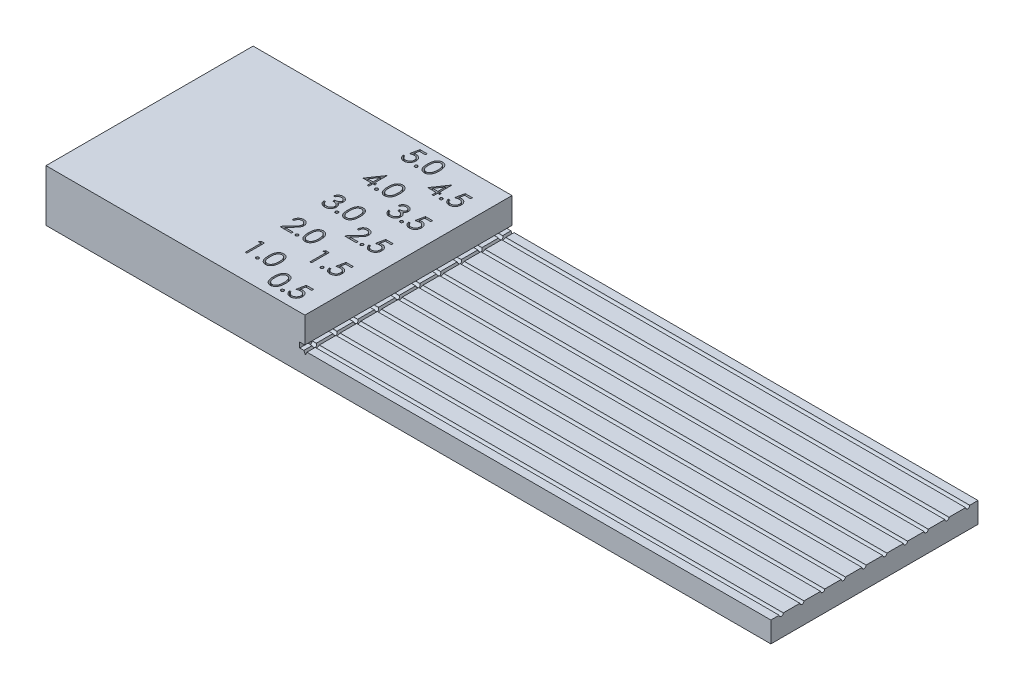
from build123d import *

# Parameters (mm, degrees)
SKETCH2_W           = 70
SKETCH2_H           = 20
BOSS_EXTRUDE1_DEPTH = 2
SKETCH3_W           = 25
SKETCH3_H           = 20
BOSS_EXTRUDE2_DEPTH = 3
CUT_EXTRUDE9_DEPTH  = 0.5
CUT_EXTRUDE6_DEPTH  = 41.620192023
CUT_EXTRUDE10_REACH = 72.887
CUT_EXTRUDE11_REACH = 72.887
SKETCH10_3_R        = 0.2
CUT_EXTRUDE12_REACH = 72.887
SKETCH10_4_R        = 0.2
CUT_EXTRUDE13_REACH = 72.887
SKETCH10_5_R        = 0.2
CUT_EXTRUDE14_REACH = 72.887
SKETCH10_6_R        = 0.2
CUT_EXTRUDE15_REACH = 72.887
SKETCH10_7_R        = 0.2
CUT_EXTRUDE16_REACH = 72.887
SKETCH10_8_R        = 0.2
CUT_EXTRUDE17_REACH = 72.887
SKETCH10_9_R        = 0.2
CUT_EXTRUDE18_REACH = 72.887
SKETCH10_10_R       = 0.2
CUT_EXTRUDE19_REACH = 72.887
SKETCH10_11_R       = 0.2
CUT_EXTRUDE7_DEPTH  = 0.5


with BuildPart() as part:
    # Sketch2 → Boss-Extrude1 (new body)
    with BuildSketch(Plane(origin=(0, 0, 0), x_dir=(1, 0, 0), z_dir=(0, 1, 0))):
        Rectangle(SKETCH2_W, SKETCH2_H)
    extrude(amount=BOSS_EXTRUDE1_DEPTH)

    # Sketch3 → Boss-Extrude2 (add)
    with BuildSketch(Plane(origin=(0, 2, 0), x_dir=(1, 0, 0), z_dir=(0, 1, 0))):
        with Locations((-22.5, 0)):
            Rectangle(SKETCH3_W, SKETCH3_H)
    extrude(amount=BOSS_EXTRUDE2_DEPTH)

    # Sketch9 → Cut-Extrude9 (cut)
    with BuildSketch(Plane(origin=(0, 2, 0), x_dir=(1, 0, 0), z_dir=(0, 1, 0))):
        Polygon((-10, -10), (-10.5, -10), (-10.5, -8), (-11.161958816, -8), (-11.161958816, -6), (-11.661958816, -6), (-11.661958816, -4), (-12.161958816, -4), (-12.161958816, -2), (-12.661958816, -2), (-12.661958816, 0), (-13.161958816, 0), (-13.161958816, 2), (-13.661958816, 2), (-13.661958816, 4), (-14.161958816, 4), (-14.161958816, 6), (-14.661958816, 6), (-14.661958816, 8), (-15.161958816, 8), (-15.161958816, 10), (-10, 10), align=None)
    extrude(amount=CUT_EXTRUDE9_DEPTH, mode=Mode.SUBTRACT)

    # Sketch6 → Cut-Extrude6 (cut, through all)
    with BuildSketch(Plane.XY.offset(10)):
        Polygon((-9.95, 1.7), (-10.1, 2), (-9.8, 2), align=None)
    extrude(amount=-CUT_EXTRUDE6_DEPTH, mode=Mode.SUBTRACT)

    # Cut-Extrude10: up to this face of the body (flat: up to its plane)
    cut_extrude10_end = Plane(part.part.faces().sort_by_distance((-10.5, 2.25, 9))[0])
    # Sketch10 → Cut-Extrude10 (cut, up to the picked face)
    with BuildSketch(Plane(origin=(35, 0, 0), x_dir=(0, 0, -1), z_dir=(1, 0, 0)), mode=Mode.PRIVATE) as cut_extrude10_sk1:
        with BuildLine():
            Line((-9.2, 2), (-8.8, 2))
            ThreePointArc((-8.8, 2), (-9, 2.2), (-9.2, 2))
        make_face()
    cut_extrude10_tool1 = split(extrude(cut_extrude10_sk1.sketch, amount=-CUT_EXTRUDE10_REACH, mode=Mode.PRIVATE), bisect_by=cut_extrude10_end, keep=Keep.BOTH, mode=Mode.PRIVATE)
    # Sketch10 → Cut-Extrude10 (cut, up to the picked face)
    with BuildSketch(Plane(origin=(35, 0, 0), x_dir=(0, 0, -1), z_dir=(1, 0, 0)), mode=Mode.PRIVATE) as cut_extrude10_sk2:
        with BuildLine():
            ThreePointArc((-9.2, 2), (-9, 1.8), (-8.8, 2))
            Line((-8.8, 2), (-9.2, 2))
        make_face()
    cut_extrude10_tool2 = split(extrude(cut_extrude10_sk2.sketch, amount=-CUT_EXTRUDE10_REACH, mode=Mode.PRIVATE), bisect_by=cut_extrude10_end, keep=Keep.BOTH, mode=Mode.PRIVATE)
    # Sketch10 → Cut-Extrude10 (cut, up to the picked face)
    with BuildSketch(Plane(origin=(35, 0, 0), x_dir=(0, 0, -1), z_dir=(1, 0, 0)), mode=Mode.PRIVATE) as cut_extrude10_sk3:
        with BuildLine():
            Line((-9.2, 2), (-8.8, 2))
            ThreePointArc((-8.8, 2), (-9, 2.2), (-9.2, 2))
        make_face()
    cut_extrude10_tool3 = split(extrude(cut_extrude10_sk3.sketch, amount=-CUT_EXTRUDE10_REACH, mode=Mode.PRIVATE), bisect_by=cut_extrude10_end, keep=Keep.BOTH, mode=Mode.PRIVATE)
    # Sketch10 → Cut-Extrude10 (cut, up to the picked face)
    with BuildSketch(Plane(origin=(35, 0, 0), x_dir=(0, 0, -1), z_dir=(1, 0, 0)), mode=Mode.PRIVATE) as cut_extrude10_sk4:
        with BuildLine():
            ThreePointArc((-9.2, 2), (-9, 1.8), (-8.8, 2))
            Line((-8.8, 2), (-9.2, 2))
        make_face()
    cut_extrude10_tool4 = split(extrude(cut_extrude10_sk4.sketch, amount=-CUT_EXTRUDE10_REACH, mode=Mode.PRIVATE), bisect_by=cut_extrude10_end, keep=Keep.BOTH, mode=Mode.PRIVATE)
    add(cut_extrude10_tool1.solids().sort_by(Axis((35, 2.084883, 9), (-1, 0, 0)))[0], mode=Mode.SUBTRACT)
    add(cut_extrude10_tool2.solids().sort_by(Axis((35, 1.915117, 9), (-1, 0, 0)))[0], mode=Mode.SUBTRACT)
    add(cut_extrude10_tool3.solids().sort_by(Axis((35, 2.084883, 9), (-1, 0, 0)))[0], mode=Mode.SUBTRACT)
    add(cut_extrude10_tool4.solids().sort_by(Axis((35, 1.915117, 9), (-1, 0, 0)))[0], mode=Mode.SUBTRACT)

    # Cut-Extrude11: up to this face of the body (flat: up to its plane)
    cut_extrude11_end = Plane(part.part.faces().sort_by_distance((-11.161958816, 2.25, 7))[0])
    # Sketch10<3> → Cut-Extrude11 (cut, up to the picked face)
    with BuildSketch(Plane(origin=(35, 0, 0), x_dir=(0, 0, -1), z_dir=(1, 0, 0)), mode=Mode.PRIVATE) as cut_extrude11_sk1:
        with Locations((-7, 2)):
            Circle(SKETCH10_3_R)
    cut_extrude11_tool1 = split(extrude(cut_extrude11_sk1.sketch, amount=-CUT_EXTRUDE11_REACH, mode=Mode.PRIVATE), bisect_by=cut_extrude11_end, keep=Keep.BOTH, mode=Mode.PRIVATE)
    add(cut_extrude11_tool1.solids().sort_by(Axis((35, 2, 7), (-1, 0, 0)))[0], mode=Mode.SUBTRACT)

    # Cut-Extrude12: up to this face of the body (flat: up to its plane)
    cut_extrude12_end = Plane(part.part.faces().sort_by_distance((-11.661958816, 2.25, 5))[0])
    # Sketch10<4> → Cut-Extrude12 (cut, up to the picked face)
    with BuildSketch(Plane(origin=(35, 0, 0), x_dir=(0, 0, -1), z_dir=(1, 0, 0)), mode=Mode.PRIVATE) as cut_extrude12_sk1:
        with Locations((-5, 2)):
            Circle(SKETCH10_4_R)
    cut_extrude12_tool1 = split(extrude(cut_extrude12_sk1.sketch, amount=-CUT_EXTRUDE12_REACH, mode=Mode.PRIVATE), bisect_by=cut_extrude12_end, keep=Keep.BOTH, mode=Mode.PRIVATE)
    add(cut_extrude12_tool1.solids().sort_by(Axis((35, 2, 5), (-1, 0, 0)))[0], mode=Mode.SUBTRACT)

    # Cut-Extrude13: up to this face of the body (flat: up to its plane)
    cut_extrude13_end = Plane(part.part.faces().sort_by_distance((-12.161958816, 2.25, 3))[0])
    # Sketch10<5> → Cut-Extrude13 (cut, up to the picked face)
    with BuildSketch(Plane(origin=(35, 0, 0), x_dir=(0, 0, -1), z_dir=(1, 0, 0)), mode=Mode.PRIVATE) as cut_extrude13_sk1:
        with Locations((-3, 2)):
            Circle(SKETCH10_5_R)
    cut_extrude13_tool1 = split(extrude(cut_extrude13_sk1.sketch, amount=-CUT_EXTRUDE13_REACH, mode=Mode.PRIVATE), bisect_by=cut_extrude13_end, keep=Keep.BOTH, mode=Mode.PRIVATE)
    add(cut_extrude13_tool1.solids().sort_by(Axis((35, 2, 3), (-1, 0, 0)))[0], mode=Mode.SUBTRACT)

    # Cut-Extrude14: up to this face of the body (flat: up to its plane)
    cut_extrude14_end = Plane(part.part.faces().sort_by_distance((-12.661958816, 2.25, 1))[0])
    # Sketch10<6> → Cut-Extrude14 (cut, up to the picked face)
    with BuildSketch(Plane(origin=(35, 0, 0), x_dir=(0, 0, -1), z_dir=(1, 0, 0)), mode=Mode.PRIVATE) as cut_extrude14_sk1:
        with Locations((-1, 2)):
            Circle(SKETCH10_6_R)
    cut_extrude14_tool1 = split(extrude(cut_extrude14_sk1.sketch, amount=-CUT_EXTRUDE14_REACH, mode=Mode.PRIVATE), bisect_by=cut_extrude14_end, keep=Keep.BOTH, mode=Mode.PRIVATE)
    add(cut_extrude14_tool1.solids().sort_by(Axis((35, 2, 1), (-1, 0, 0)))[0], mode=Mode.SUBTRACT)

    # Cut-Extrude15: up to this face of the body (flat: up to its plane)
    cut_extrude15_end = Plane(part.part.faces().sort_by_distance((-13.161958816, 2.25, -1))[0])
    # Sketch10<7> → Cut-Extrude15 (cut, up to the picked face)
    with BuildSketch(Plane(origin=(35, 0, 0), x_dir=(0, 0, -1), z_dir=(1, 0, 0)), mode=Mode.PRIVATE) as cut_extrude15_sk1:
        with Locations((1, 2)):
            Circle(SKETCH10_7_R)
    cut_extrude15_tool1 = split(extrude(cut_extrude15_sk1.sketch, amount=-CUT_EXTRUDE15_REACH, mode=Mode.PRIVATE), bisect_by=cut_extrude15_end, keep=Keep.BOTH, mode=Mode.PRIVATE)
    add(cut_extrude15_tool1.solids().sort_by(Axis((35, 2, -1), (-1, 0, 0)))[0], mode=Mode.SUBTRACT)

    # Cut-Extrude16: up to this face of the body (flat: up to its plane)
    cut_extrude16_end = Plane(part.part.faces().sort_by_distance((-13.661958816, 2.25, -3))[0])
    # Sketch10<8> → Cut-Extrude16 (cut, up to the picked face)
    with BuildSketch(Plane(origin=(35, 0, 0), x_dir=(0, 0, -1), z_dir=(1, 0, 0)), mode=Mode.PRIVATE) as cut_extrude16_sk1:
        with Locations((3, 2)):
            Circle(SKETCH10_8_R)
    cut_extrude16_tool1 = split(extrude(cut_extrude16_sk1.sketch, amount=-CUT_EXTRUDE16_REACH, mode=Mode.PRIVATE), bisect_by=cut_extrude16_end, keep=Keep.BOTH, mode=Mode.PRIVATE)
    add(cut_extrude16_tool1.solids().sort_by(Axis((35, 2, -3), (-1, 0, 0)))[0], mode=Mode.SUBTRACT)

    # Cut-Extrude17: up to this face of the body (flat: up to its plane)
    cut_extrude17_end = Plane(part.part.faces().sort_by_distance((-14.161958816, 2.25, -5))[0])
    # Sketch10<9> → Cut-Extrude17 (cut, up to the picked face)
    with BuildSketch(Plane(origin=(35, 0, 0), x_dir=(0, 0, -1), z_dir=(1, 0, 0)), mode=Mode.PRIVATE) as cut_extrude17_sk1:
        with Locations((5, 2)):
            Circle(SKETCH10_9_R)
    cut_extrude17_tool1 = split(extrude(cut_extrude17_sk1.sketch, amount=-CUT_EXTRUDE17_REACH, mode=Mode.PRIVATE), bisect_by=cut_extrude17_end, keep=Keep.BOTH, mode=Mode.PRIVATE)
    add(cut_extrude17_tool1.solids().sort_by(Axis((35, 2, -5), (-1, 0, 0)))[0], mode=Mode.SUBTRACT)

    # Cut-Extrude18: up to this face of the body (flat: up to its plane)
    cut_extrude18_end = Plane(part.part.faces().sort_by_distance((-14.661958816, 2.25, -7))[0])
    # Sketch10<10> → Cut-Extrude18 (cut, up to the picked face)
    with BuildSketch(Plane(origin=(35, 0, 0), x_dir=(0, 0, -1), z_dir=(1, 0, 0)), mode=Mode.PRIVATE) as cut_extrude18_sk1:
        with Locations((7, 2)):
            Circle(SKETCH10_10_R)
    cut_extrude18_tool1 = split(extrude(cut_extrude18_sk1.sketch, amount=-CUT_EXTRUDE18_REACH, mode=Mode.PRIVATE), bisect_by=cut_extrude18_end, keep=Keep.BOTH, mode=Mode.PRIVATE)
    add(cut_extrude18_tool1.solids().sort_by(Axis((35, 2, -7), (-1, 0, 0)))[0], mode=Mode.SUBTRACT)

    # Cut-Extrude19: up to this face of the body (flat: up to its plane)
    cut_extrude19_end = Plane(part.part.faces().sort_by_distance((-15.161958816, 2.25, -9))[0])
    # Sketch10<11> → Cut-Extrude19 (cut, up to the picked face)
    with BuildSketch(Plane(origin=(35, 0, 0), x_dir=(0, 0, -1), z_dir=(1, 0, 0)), mode=Mode.PRIVATE) as cut_extrude19_sk1:
        with Locations((9, 2)):
            Circle(SKETCH10_11_R)
    cut_extrude19_tool1 = split(extrude(cut_extrude19_sk1.sketch, amount=-CUT_EXTRUDE19_REACH, mode=Mode.PRIVATE), bisect_by=cut_extrude19_end, keep=Keep.BOTH, mode=Mode.PRIVATE)
    add(cut_extrude19_tool1.solids().sort_by(Axis((35, 2, -9), (-1, 0, 0)))[0], mode=Mode.SUBTRACT)

    # Sketch7 → Cut-Extrude7 (cut)
    # profile 1 of 30: a face of its own
    with BuildSketch(Plane(origin=(0, 5, 0), x_dir=(1, 0, 0), z_dir=(0, 1, 0))):
        with BuildLine():
            Line((-17.586220044, 9.4), (-17.586220044, 9.225641026))
            Line((-17.586220044, 9.225641026), (-18.164465236, 9.225641026))
            Line((-18.164465236, 9.225641026), (-18.256071806, 8.778505609))
            add(Edge.make_bspline(
                [(-18.256071806, 8.778505609), (-18.238073239, 8.783474598), (-18.203203861, 8.793101229), (-18.151737643, 8.803789746), (-18.102878572, 8.810232962), (-18.071173393, 8.811112741), (-18.055831422, 8.811538462)],
                knots=[0, 0, 0, 0, 1.100273476, 2.13160584, 3.095893838, 4, 4, 4, 4], degree=3))
            add(Edge.make_bspline(
                [(-18.055831422, 8.811538462), (-18.036847891, 8.811127578), (-17.999521527, 8.81031968), (-17.944908324, 8.802561924), (-17.892775204, 8.790351109), (-17.843231196, 8.773292569), (-17.796184643, 8.751479271), (-17.752068399, 8.724230728), (-17.710220269, 8.692400253), (-17.67139101, 8.655804104), (-17.636164917, 8.61552789), (-17.605192865, 8.572222639), (-17.578885321, 8.526309203), (-17.55772724, 8.477348907), (-17.540831992, 8.425883033), (-17.529586737, 8.371370064), (-17.522098622, 8.314323834), (-17.521262034, 8.275318757), (-17.520835428, 8.255428686)],
                knots=[0, 0, 0, 0, 1.052922333, 2.070308379, 3.05430497, 4.020497103, 4.973039431, 5.925935799, 6.892292201, 7.88610001, 8.88166317, 9.857072816, 10.836096531, 11.812156883, 12.81219415, 13.836441305, 14.89672472, 16, 16, 16, 16], degree=3))
            add(Edge.make_bspline(
                [(-17.520835428, 8.255428686), (-17.521158465, 8.241575036), (-17.521800172, 8.214054956), (-17.525063486, 8.173184916), (-17.531346548, 8.133180111), (-17.5397823, 8.094035235), (-17.550731475, 8.055824397), (-17.563986158, 8.018438227), (-17.580207086, 7.982109418), (-17.597999468, 7.946494226), (-17.618033471, 7.912397808), (-17.640268746, 7.880511157), (-17.663760556, 7.850355935), (-17.689037801, 7.82225555), (-17.716335427, 7.796394656), (-17.745322839, 7.772619776), (-17.775768732, 7.750528845), (-17.808144135, 7.731018578), (-17.841727627, 7.713065142), (-17.877004189, 7.698336567), (-17.913170815, 7.685168596), (-17.950748041, 7.67467254), (-17.98965075, 7.666448157), (-18.029943069, 7.660862151), (-18.07141368, 7.656793595), (-18.099524401, 7.656538908), (-18.11372405, 7.656410256)],
                knots=[0, 0, 0, 0, 1.056347294, 2.098418968, 3.122841568, 4.141288669, 5.149314143, 6.15115421, 7.162517403, 8.180376062, 9.185164535, 10.17417709, 11.141909838, 12.097768115, 13.052685741, 14.0056014, 14.954263652, 15.917497458, 16.885230207, 17.854509472, 18.828990115, 19.81800267, 20.826176721, 21.857883937, 22.917946725, 24, 24, 24, 24], degree=3))
            add(Edge.make_bspline(
                [(-18.11372405, 7.656410256), (-18.130662938, 7.656745806), (-18.163988198, 7.657405961), (-18.212812474, 7.664312082), (-18.259788139, 7.674203128), (-18.304537046, 7.689083601), (-18.347460231, 7.707728859), (-18.387979837, 7.731293856), (-18.427131214, 7.757997993), (-18.463322774, 7.789511307), (-18.496912887, 7.823956067), (-18.526981762, 7.861335492), (-18.553760928, 7.90103265), (-18.576821548, 7.943240325), (-18.596492016, 7.987847611), (-18.61194501, 8.03502164), (-18.624417354, 8.084515928), (-18.629693872, 8.11859049), (-18.63237389, 8.135897436)],
                knots=[0, 0, 0, 0, 1.0467383, 2.05933395, 3.04377827, 4.011590433, 4.970194871, 5.932262533, 6.905835911, 7.896367577, 8.894135286, 9.877477877, 10.858688626, 11.851381753, 12.8477658, 13.868841284, 14.917554742, 16, 16, 16, 16], degree=3))
            Line((-18.63237389, 8.135897436), (-18.479809787, 8.135897436))
            add(Edge.make_bspline(
                [(-18.479809787, 8.135897436), (-18.476055916, 8.119686016), (-18.468840768, 8.088526767), (-18.453003691, 8.044748687), (-18.433640265, 8.005736493), (-18.410615296, 7.970974124), (-18.383148138, 7.940661182), (-18.351805273, 7.913647181), (-18.31666495, 7.889276404), (-18.27761681, 7.868962488), (-18.236421886, 7.851637665), (-18.193306384, 7.840101127), (-18.149444273, 7.831989265), (-18.119777636, 7.831177267), (-18.104869883, 7.830769231)],
                knots=[0, 0, 0, 0, 1.136247022, 2.183929868, 3.172523383, 4.106158343, 5.02341133, 5.958108904, 6.928429099, 7.938127109, 8.96079061, 9.975095812, 10.982467395, 12, 12, 12, 12], degree=3))
            add(Edge.make_bspline(
                [(-18.104869883, 7.830769231), (-18.090318639, 7.831167894), (-18.06166712, 7.831952866), (-18.019501589, 7.837994672), (-17.978792479, 7.847299778), (-17.939941477, 7.861225136), (-17.902268729, 7.878149714), (-17.866727183, 7.899868465), (-17.832288643, 7.924863331), (-17.80002355, 7.953499408), (-17.77047296, 7.985056117), (-17.744362844, 8.01880228), (-17.722614057, 8.054801891), (-17.704286062, 8.092431708), (-17.690368745, 8.13210415), (-17.680440268, 8.173633292), (-17.674610211, 8.217121711), (-17.67380821, 8.246783947), (-17.673399531, 8.261899038)],
                knots=[0, 0, 0, 0, 1.027316725, 2.022795036, 3.002884548, 3.971462791, 4.93288096, 5.914575861, 6.907176829, 7.935150275, 8.956128384, 9.956726525, 10.942570165, 11.921478529, 12.907843606, 13.90538589, 14.932640048, 16, 16, 16, 16], degree=3))
            add(Edge.make_bspline(
                [(-17.673399531, 8.261899038), (-17.673719364, 8.275535832), (-17.674345391, 8.302227915), (-17.679460239, 8.341278958), (-17.688357055, 8.378228722), (-17.700705796, 8.413255636), (-17.716384414, 8.446392736), (-17.735544052, 8.477674222), (-17.758544274, 8.506687799), (-17.784817477, 8.533447039), (-17.813599954, 8.558143121), (-17.845386914, 8.579195963), (-17.879513165, 8.596907009), (-17.915567541, 8.612191465), (-17.954407635, 8.62316897), (-17.995264285, 8.631410514), (-18.038578686, 8.636177976), (-18.06819302, 8.636839465), (-18.083415556, 8.637179487)],
                knots=[0, 0, 0, 0, 1.045622112, 2.046656509, 3.013763289, 3.955457236, 4.890082067, 5.820317437, 6.762574623, 7.722996705, 8.69280354, 9.665887285, 10.63943826, 11.638615906, 12.663482002, 13.728887084, 14.832589034, 16, 16, 16, 16], degree=3))
            add(Edge.make_bspline(
                [(-18.083415556, 8.637179487), (-18.096592465, 8.636897486), (-18.123799437, 8.636315224), (-18.165533382, 8.632028069), (-18.209389361, 8.62511184), (-18.255199259, 8.61559852), (-18.303100649, 8.60314914), (-18.352992444, 8.588230668), (-18.404979544, 8.570394269), (-18.440008153, 8.556924336), (-18.458014915, 8.55)],
                knots=[0, 0, 0, 0, 0.817624296, 1.688186739, 2.600797293, 3.572016777, 4.590301741, 5.671205678, 6.80286297, 8, 8, 8, 8], degree=3))
            Line((-18.458014915, 8.55), (-18.283655941, 9.4))
            Line((-18.283655941, 9.4), (-17.586220044, 9.4))
        make_face()
    # profile 2 of 30: a face of its own
    with BuildSketch(Plane(origin=(0, 5, 0), x_dir=(1, 0, 0), z_dir=(0, 1, 0))):
        with BuildLine():
            add(Edge.make_bspline(
                [(-17.074040556, 7.961538462), (-17.064573882, 7.960975923), (-17.046015573, 7.959873133), (-17.01918514, 7.95230732), (-16.994902019, 7.938873114), (-16.973272072, 7.920968336), (-16.955443212, 7.899259014), (-16.941530241, 7.875169572), (-16.934030334, 7.848114513), (-16.932935576, 7.829448671), (-16.93237389, 7.819871795)],
                knots=[0, 0, 0, 0, 1.020151414, 1.999887582, 2.974338812, 3.990962822, 5.007586832, 5.987933904, 6.967670073, 8, 8, 8, 8], degree=3))
            add(Edge.make_bspline(
                [(-16.93237389, 7.819871795), (-16.93295461, 7.810525035), (-16.934099782, 7.792093361), (-16.941513049, 7.765242365), (-16.955549245, 7.741137868), (-16.973149098, 7.719133973), (-16.994907366, 7.701191264), (-17.019242549, 7.687871354), (-17.045952588, 7.679763821), (-17.064563374, 7.678731048), (-17.074040556, 7.678205128)],
                knots=[0, 0, 0, 0, 1.009421747, 1.99056486, 2.972319754, 3.999869655, 5.017953583, 5.993804169, 6.978383603, 8, 8, 8, 8], degree=3))
            add(Edge.make_bspline(
                [(-17.074040556, 7.678205128), (-17.083524568, 7.678712018), (-17.102039842, 7.6797016), (-17.128650182, 7.688037821), (-17.153133567, 7.701066358), (-17.174887598, 7.719167429), (-17.192634856, 7.741024641), (-17.206052899, 7.765408371), (-17.214110971, 7.792016498), (-17.215170738, 7.810509896), (-17.215707223, 7.819871795)],
                knots=[0, 0, 0, 0, 1.022052826, 1.995314843, 2.982371812, 4.00089066, 5.028879526, 6.005146991, 6.990147033, 8, 8, 8, 8], degree=3))
            add(Edge.make_bspline(
                [(-17.215707223, 7.819871795), (-17.215191346, 7.829464351), (-17.21418416, 7.848192639), (-17.206035982, 7.875003634), (-17.192738965, 7.899371161), (-17.174764916, 7.920935215), (-17.15313883, 7.938997619), (-17.128709244, 7.952143375), (-17.101975753, 7.959934433), (-17.083513783, 7.960994512), (-17.074040556, 7.961538462)],
                knots=[0, 0, 0, 0, 1.032775665, 2.016367738, 2.991239715, 4.008302682, 5.025365648, 6.011011707, 6.979408107, 8, 8, 8, 8], degree=3))
        make_face()
    # profile 3 of 30: a face of its own
    with BuildSketch(Plane(origin=(0, 5, 0), x_dir=(1, 0, 0), z_dir=(0, 1, 0))):
        with BuildLine():
            add(Edge.make_bspline(
                [(-16.714425172, 8.54931891), (-16.714265849, 8.576566213), (-16.713956361, 8.629494491), (-16.710513414, 8.70661846), (-16.704793962, 8.7789706), (-16.696955809, 8.846554375), (-16.687417362, 8.909387232), (-16.674684126, 8.967301257), (-16.660203621, 9.020564495), (-16.643421005, 9.069350633), (-16.624484079, 9.114316945), (-16.603873152, 9.1562949), (-16.580770252, 9.195220982), (-16.556495751, 9.23171648), (-16.530067031, 9.265183989), (-16.50223619, 9.296096139), (-16.471916993, 9.323738504), (-16.440140103, 9.348920993), (-16.40661782, 9.370996451), (-16.372305668, 9.390440924), (-16.336967474, 9.407052288), (-16.300506757, 9.420113357), (-16.263251228, 9.430901483), (-16.225070653, 9.438278972), (-16.185901991, 9.442920899), (-16.159463865, 9.44336468), (-16.146055781, 9.443589744)],
                knots=[0, 0, 0, 0, 1.646270934, 3.197905019, 4.663502075, 6.030701355, 7.308322542, 8.50163776, 9.611534131, 10.641858119, 11.616356847, 12.558055219, 13.465016945, 14.349605745, 15.204443733, 16.039544428, 16.859896111, 17.680448484, 18.487036065, 19.28249412, 20.06191084, 20.843045899, 21.620316918, 22.403196591, 23.190181807, 24, 24, 24, 24], degree=3))
            add(Edge.make_bspline(
                [(-16.146055781, 9.443589744), (-16.132535691, 9.443352805), (-16.105648487, 9.442881608), (-16.065897448, 9.438352836), (-16.027064745, 9.43083829), (-15.989315935, 9.42019096), (-15.952340941, 9.406981631), (-15.916428972, 9.390425032), (-15.881356961, 9.371152439), (-15.84768225, 9.348506556), (-15.815035151, 9.323258021), (-15.784217569, 9.294716154), (-15.755226699, 9.263169147), (-15.727698693, 9.228954528), (-15.702414546, 9.191416058), (-15.678336022, 9.151206633), (-15.65678389, 9.10762307), (-15.636027048, 9.061392557), (-15.618110511, 9.011235923), (-15.601952621, 8.957435896), (-15.588897122, 8.899357006), (-15.578022332, 8.837303972), (-15.569597668, 8.771048909), (-15.563461814, 8.700733841), (-15.560220601, 8.626312509), (-15.559610203, 8.575430125), (-15.559296967, 8.54931891)],
                knots=[0, 0, 0, 0, 0.810914788, 1.612654377, 2.396697861, 3.181598691, 3.963628158, 4.749916497, 5.551656086, 6.361998678, 7.18212741, 8.025565596, 8.878627764, 9.750805457, 10.657531673, 11.591944965, 12.560506719, 13.57287815, 14.630710178, 15.753379473, 16.941251878, 18.199788006, 19.531962791, 20.947069417, 22.433333509, 24, 24, 24, 24], degree=3))
            add(Edge.make_bspline(
                [(-15.559296967, 8.54931891), (-15.559613451, 8.523321584), (-15.560230107, 8.472666853), (-15.563425478, 8.398580379), (-15.569719671, 8.328638472), (-15.577593094, 8.26267339), (-15.588497847, 8.20095969), (-15.601906071, 8.143283815), (-15.61679337, 8.089396694), (-15.63517027, 8.039739786), (-15.655284044, 7.993620378), (-15.677167996, 7.950553477), (-15.70061334, 7.910158421), (-15.726156445, 7.872758543), (-15.753382389, 7.83808891), (-15.782873886, 7.806761493), (-15.813799599, 7.778021453), (-15.846542772, 7.752447805), (-15.880742669, 7.730063757), (-15.91569422, 7.710045601), (-15.952017578, 7.693904006), (-15.988889584, 7.680044129), (-16.026837647, 7.669455338), (-16.065814465, 7.662133751), (-16.10562178, 7.656998854), (-16.132531112, 7.656607135), (-16.146055781, 7.656410256)],
                knots=[0, 0, 0, 0, 1.561518951, 3.042555995, 4.452378317, 5.7783523, 7.031515105, 8.214008947, 9.334062868, 10.386615937, 11.391082383, 12.354592575, 13.286541444, 14.194233754, 15.072674879, 15.931287219, 16.775624067, 17.606195743, 18.42308326, 19.229000347, 20.022332153, 20.807536673, 21.593273796, 22.3848459, 23.188221202, 24, 24, 24, 24], degree=3))
            add(Edge.make_bspline(
                [(-16.146055781, 7.656410256), (-16.159463493, 7.656636772), (-16.185900885, 7.657083416), (-16.225074921, 7.661704372), (-16.263097822, 7.669133616), (-16.300157216, 7.679535967), (-16.336443238, 7.692268887), (-16.371461434, 7.708857819), (-16.405601167, 7.727962938), (-16.438771351, 7.749720714), (-16.470348686, 7.774648389), (-16.500510866, 7.802219615), (-16.528500161, 7.833122415), (-16.554551007, 7.866868835), (-16.57930985, 7.903148409), (-16.602084689, 7.942456476), (-16.623150532, 7.984637173), (-16.642405942, 8.029963015), (-16.65947815, 8.079095409), (-16.674558465, 8.132596438), (-16.686465342, 8.190938319), (-16.696657063, 8.253652468), (-16.704877477, 8.321008377), (-16.710489578, 8.393042613), (-16.713958217, 8.469710285), (-16.71426668, 8.522298462), (-16.714425172, 8.54931891)],
                knots=[0, 0, 0, 0, 0.810891512, 1.598919785, 2.382837074, 3.152667961, 3.926044502, 4.706494248, 5.493654104, 6.291793342, 7.103789334, 7.925228297, 8.761435821, 9.622817696, 10.50288917, 11.416980706, 12.369136599, 13.353924996, 14.394355917, 15.514179734, 16.714354668, 17.994756427, 19.357759367, 20.818452758, 22.365282078, 24, 24, 24, 24], degree=3))
        make_face()
        with BuildLine():
            add(Edge.make_bspline(
                [(-16.561861069, 8.55), (-16.561803052, 8.527293489), (-16.561690452, 8.48322461), (-16.558748869, 8.419186455), (-16.554741614, 8.359458009), (-16.549572983, 8.303963435), (-16.541897266, 8.252890571), (-16.533296826, 8.205888154), (-16.522830611, 8.163204924), (-16.510447316, 8.124547988), (-16.496342612, 8.089261297), (-16.480942621, 8.056426422), (-16.464398842, 8.025655481), (-16.445883826, 7.997224871), (-16.425719366, 7.971041877), (-16.404360926, 7.946643073), (-16.381011385, 7.924884539), (-16.348709567, 7.898788638), (-16.306065566, 7.871822202), (-16.25233563, 7.848339815), (-16.19712524, 7.833582622), (-16.159651775, 7.831705941), (-16.140947608, 7.830769231)],
                knots=[0, 0, 0, 0, 1.459021318, 2.831673884, 4.118529203, 5.306027144, 6.411944654, 7.436330062, 8.375795394, 9.233974572, 10.042671642, 10.816086306, 11.563610507, 12.285937304, 12.993564865, 13.685989202, 14.367179055, 15.041617293, 16.353048772, 17.594441528, 18.799311195, 20, 20, 20, 20], degree=3))
            add(Edge.make_bspline(
                [(-16.140947608, 7.830769231), (-16.122122453, 7.831545296), (-16.08451101, 7.833095823), (-16.02956031, 7.84805521), (-15.976214179, 7.870626129), (-15.934407808, 7.897314918), (-15.902602001, 7.922731535), (-15.879813748, 7.944401507), (-15.858897896, 7.968665785), (-15.839060317, 7.994845443), (-15.820865909, 8.02344065), (-15.804320956, 8.054313901), (-15.78922333, 8.08755093), (-15.780621794, 8.110753375), (-15.77622405, 8.122616186)],
                knots=[0, 0, 0, 0, 1.353760809, 2.704726607, 4.075137775, 5.516104923, 6.260822281, 7.007110065, 7.778089737, 8.566572457, 9.372053459, 10.217411131, 11.088608312, 12, 12, 12, 12], degree=3))
            add(Edge.make_bspline(
                [(-15.77622405, 8.122616186), (-15.771098906, 8.137784916), (-15.760692665, 8.168583945), (-15.747281231, 8.216360576), (-15.73671918, 8.266487633), (-15.727216974, 8.318665546), (-15.720731204, 8.373279116), (-15.715510838, 8.430159359), (-15.712435933, 8.489349164), (-15.712054768, 8.529563874), (-15.711861069, 8.55)],
                knots=[0, 0, 0, 0, 0.884706709, 1.796334032, 2.740027952, 3.714592787, 4.726048262, 5.777819803, 6.87074269, 8, 8, 8, 8], degree=3))
            add(Edge.make_bspline(
                [(-15.711861069, 8.55), (-15.712128304, 8.570432821), (-15.712651072, 8.610403787), (-15.714649295, 8.668941189), (-15.719809317, 8.724539815), (-15.725540317, 8.777439188), (-15.733990396, 8.827346478), (-15.743101331, 8.874679483), (-15.75534192, 8.91885181), (-15.768417239, 8.960555035), (-15.783382288, 8.999315353), (-15.799855645, 9.035313478), (-15.817449071, 9.068723201), (-15.836558159, 9.099452858), (-15.856956062, 9.127640094), (-15.879181157, 9.152719754), (-15.902351853, 9.175469138), (-15.934805915, 9.201436672), (-15.977293427, 9.227913781), (-16.030161313, 9.252280007), (-16.085178483, 9.266272607), (-16.122371303, 9.268245426), (-16.140947608, 9.269230769)],
                knots=[0, 0, 0, 0, 1.31362396, 2.569729283, 3.763502607, 4.902122613, 5.988968491, 7.01645872, 7.998833611, 8.933434873, 9.825090667, 10.667526885, 11.477055099, 12.250526234, 12.991942729, 13.710640831, 14.402115721, 15.076753259, 16.378508321, 17.609869233, 18.806226677, 20, 20, 20, 20], degree=3))
            add(Edge.make_bspline(
                [(-16.140947608, 9.269230769), (-16.159749895, 9.268244067), (-16.197388724, 9.266268864), (-16.25297773, 9.252332141), (-16.306262701, 9.228040129), (-16.34863786, 9.201348976), (-16.381114557, 9.175927511), (-16.403983293, 9.153882662), (-16.42542572, 9.129768767), (-16.445178603, 9.103344979), (-16.463679112, 9.074947515), (-16.480669889, 9.044352972), (-16.495978307, 9.01140631), (-16.510105081, 8.97613547), (-16.52252615, 8.937481868), (-16.532771789, 8.894851214), (-16.542236929, 8.847998295), (-16.548937488, 8.79664882), (-16.55489417, 8.741140345), (-16.558722253, 8.681262791), (-16.561700292, 8.617117235), (-16.561806404, 8.5728205), (-16.561861069, 8.55)],
                knots=[0, 0, 0, 0, 1.207732386, 2.417664972, 3.655092373, 4.956220595, 5.625982001, 6.301752483, 6.994047911, 7.697131622, 8.419323945, 9.170223765, 9.943494443, 10.752040957, 11.610060368, 12.549350801, 13.567764191, 14.679664412, 15.874934091, 17.154273443, 18.533957287, 20, 20, 20, 20], degree=3))
        make_face(mode=Mode.SUBTRACT)
    # profile 4 of 30: a face of its own
    with BuildSketch(Plane(origin=(0, 5, 0), x_dir=(1, 0, 0), z_dir=(0, 1, 0))):
        Polygon((-17.726183986, 5.61025641), (-17.695194403, 5.61025641), (-17.695194403, 4.433333333), (-17.499040556, 4.433333333), (-17.499040556, 4.258974359), (-17.695194403, 4.258974359), (-17.695194403, 3.866666667), (-17.847758505, 3.866666667), (-17.847758505, 4.258974359), (-18.654168762, 4.258974359), align=None)
        Polygon((-17.847758505, 4.433333333), (-17.847758505, 5.171634615), (-18.354489274, 4.433333333), align=None, mode=Mode.SUBTRACT)
    # profile 5 of 30: a face of its own
    with BuildSketch(Plane(origin=(0, 5, 0), x_dir=(1, 0, 0), z_dir=(0, 1, 0))):
        with BuildLine():
            add(Edge.make_bspline(
                [(-17.074040556, 4.128205128), (-17.064573882, 4.12764259), (-17.046015573, 4.1265398), (-17.01918514, 4.118973987), (-16.994902019, 4.10553978), (-16.973272072, 4.087635002), (-16.955443212, 4.06592568), (-16.941530241, 4.041836239), (-16.934030334, 4.01478118), (-16.932935576, 3.996115338), (-16.93237389, 3.986538462)],
                knots=[0, 0, 0, 0, 1.020151414, 1.999887582, 2.974338812, 3.990962822, 5.007586832, 5.987933904, 6.967670073, 8, 8, 8, 8], degree=3))
            add(Edge.make_bspline(
                [(-16.93237389, 3.986538462), (-16.93295461, 3.977191701), (-16.934099782, 3.958760028), (-16.941513049, 3.931909031), (-16.955549245, 3.907804535), (-16.973149098, 3.885800639), (-16.994907366, 3.867857931), (-17.019242549, 3.85453802), (-17.045952588, 3.846430487), (-17.064563374, 3.845397714), (-17.074040556, 3.844871795)],
                knots=[0, 0, 0, 0, 1.009421747, 1.99056486, 2.972319754, 3.999869655, 5.017953583, 5.993804169, 6.978383603, 8, 8, 8, 8], degree=3))
            add(Edge.make_bspline(
                [(-17.074040556, 3.844871795), (-17.083524568, 3.845378685), (-17.102039842, 3.846368267), (-17.128650182, 3.854704487), (-17.153133567, 3.867733025), (-17.174887598, 3.885834095), (-17.192634856, 3.907691308), (-17.206052899, 3.932075038), (-17.214110971, 3.958683164), (-17.215170738, 3.977176562), (-17.215707223, 3.986538462)],
                knots=[0, 0, 0, 0, 1.022052826, 1.995314843, 2.982371812, 4.00089066, 5.028879526, 6.005146991, 6.990147033, 8, 8, 8, 8], degree=3))
            add(Edge.make_bspline(
                [(-17.215707223, 3.986538462), (-17.215191346, 3.996131017), (-17.21418416, 4.014859305), (-17.206035982, 4.0416703), (-17.192738965, 4.066037828), (-17.174764916, 4.087601881), (-17.15313883, 4.105664285), (-17.128709244, 4.118810042), (-17.101975753, 4.126601099), (-17.083513783, 4.127661179), (-17.074040556, 4.128205128)],
                knots=[0, 0, 0, 0, 1.032775665, 2.016367738, 2.991239715, 4.008302682, 5.025365648, 6.011011707, 6.979408107, 8, 8, 8, 8], degree=3))
        make_face()
    # profile 6 of 30: a face of its own
    with BuildSketch(Plane(origin=(0, 5, 0), x_dir=(1, 0, 0), z_dir=(0, 1, 0))):
        with BuildLine():
            add(Edge.make_bspline(
                [(-16.714425172, 4.715985577), (-16.714265849, 4.74323288), (-16.713956361, 4.796161158), (-16.710513414, 4.873285127), (-16.704793962, 4.945637267), (-16.696955809, 5.013221042), (-16.687417362, 5.076053899), (-16.674684126, 5.133967924), (-16.660203621, 5.187231161), (-16.643421005, 5.236017299), (-16.624484079, 5.280983612), (-16.603873152, 5.322961567), (-16.580770252, 5.361887648), (-16.556495751, 5.398383147), (-16.530067031, 5.431850656), (-16.50223619, 5.462762806), (-16.471916993, 5.49040517), (-16.440140103, 5.51558766), (-16.40661782, 5.537663118), (-16.372305668, 5.557107591), (-16.336967474, 5.573718955), (-16.300506757, 5.586780024), (-16.263251228, 5.597568149), (-16.225070653, 5.604945638), (-16.185901991, 5.609587565), (-16.159463865, 5.610031347), (-16.146055781, 5.61025641)],
                knots=[0, 0, 0, 0, 1.646270934, 3.197905019, 4.663502075, 6.030701355, 7.308322542, 8.50163776, 9.611534131, 10.641858119, 11.616356847, 12.558055219, 13.465016945, 14.349605745, 15.204443733, 16.039544428, 16.859896111, 17.680448484, 18.487036065, 19.28249412, 20.06191084, 20.843045899, 21.620316918, 22.403196591, 23.190181807, 24, 24, 24, 24], degree=3))
            add(Edge.make_bspline(
                [(-16.146055781, 5.61025641), (-16.132535691, 5.610019471), (-16.105648487, 5.609548275), (-16.065897448, 5.605019503), (-16.027064745, 5.597504957), (-15.989315935, 5.586857627), (-15.952340941, 5.573648298), (-15.916428972, 5.557091698), (-15.881356961, 5.537819106), (-15.84768225, 5.515173222), (-15.815035151, 5.489924688), (-15.784217569, 5.46138282), (-15.755226699, 5.429835814), (-15.727698693, 5.395621194), (-15.702414546, 5.358082725), (-15.678336022, 5.3178733), (-15.65678389, 5.274289737), (-15.636027048, 5.228059224), (-15.618110511, 5.17790259), (-15.601952621, 5.124102563), (-15.588897122, 5.066023672), (-15.578022332, 5.003970639), (-15.569597668, 4.937715576), (-15.563461814, 4.867400508), (-15.560220601, 4.792979175), (-15.559610203, 4.742096792), (-15.559296967, 4.715985577)],
                knots=[0, 0, 0, 0, 0.810914788, 1.612654377, 2.396697861, 3.181598691, 3.963628158, 4.749916497, 5.551656086, 6.361998678, 7.18212741, 8.025565596, 8.878627764, 9.750805457, 10.657531673, 11.591944965, 12.560506719, 13.57287815, 14.630710178, 15.753379473, 16.941251878, 18.199788006, 19.531962791, 20.947069417, 22.433333509, 24, 24, 24, 24], degree=3))
            add(Edge.make_bspline(
                [(-15.559296967, 4.715985577), (-15.559613451, 4.68998825), (-15.560230107, 4.639333519), (-15.563425478, 4.565247046), (-15.569719671, 4.495305139), (-15.577593094, 4.429340057), (-15.588497847, 4.367626356), (-15.601906071, 4.309950482), (-15.61679337, 4.256063361), (-15.63517027, 4.206406453), (-15.655284044, 4.160287044), (-15.677167996, 4.117220144), (-15.70061334, 4.076825087), (-15.726156445, 4.03942521), (-15.753382389, 4.004755577), (-15.782873886, 3.97342816), (-15.813799599, 3.944688119), (-15.846542772, 3.919114472), (-15.880742669, 3.896730424), (-15.91569422, 3.876712268), (-15.952017578, 3.860570673), (-15.988889584, 3.846710796), (-16.026837647, 3.836122005), (-16.065814465, 3.828800418), (-16.10562178, 3.82366552), (-16.132531112, 3.823273802), (-16.146055781, 3.823076923)],
                knots=[0, 0, 0, 0, 1.561518951, 3.042555995, 4.452378317, 5.7783523, 7.031515105, 8.214008947, 9.334062868, 10.386615937, 11.391082383, 12.354592575, 13.286541444, 14.194233754, 15.072674879, 15.931287219, 16.775624067, 17.606195743, 18.42308326, 19.229000347, 20.022332153, 20.807536673, 21.593273796, 22.3848459, 23.188221202, 24, 24, 24, 24], degree=3))
            add(Edge.make_bspline(
                [(-16.146055781, 3.823076923), (-16.159463493, 3.823303439), (-16.185900885, 3.823750083), (-16.225074921, 3.828371038), (-16.263097822, 3.835800283), (-16.300157216, 3.846202633), (-16.336443238, 3.858935554), (-16.371461434, 3.875524486), (-16.405601167, 3.894629605), (-16.438771351, 3.916387381), (-16.470348686, 3.941315056), (-16.500510866, 3.968886282), (-16.528500161, 3.999789081), (-16.554551007, 4.033535501), (-16.57930985, 4.069815076), (-16.602084689, 4.109123143), (-16.623150532, 4.15130384), (-16.642405942, 4.196629682), (-16.65947815, 4.245762075), (-16.674558465, 4.299263105), (-16.686465342, 4.357604985), (-16.696657063, 4.420319135), (-16.704877477, 4.487675044), (-16.710489578, 4.559709279), (-16.713958217, 4.636376952), (-16.71426668, 4.688965128), (-16.714425172, 4.715985577)],
                knots=[0, 0, 0, 0, 0.810891512, 1.598919785, 2.382837074, 3.152667961, 3.926044502, 4.706494248, 5.493654104, 6.291793342, 7.103789334, 7.925228297, 8.761435821, 9.622817696, 10.50288917, 11.416980706, 12.369136599, 13.353924996, 14.394355917, 15.514179734, 16.714354668, 17.994756427, 19.357759367, 20.818452758, 22.365282078, 24, 24, 24, 24], degree=3))
        make_face()
        with BuildLine():
            add(Edge.make_bspline(
                [(-16.561861069, 4.716666667), (-16.561803052, 4.693960156), (-16.561690452, 4.649891277), (-16.558748869, 4.585853122), (-16.554741614, 4.526124676), (-16.549572983, 4.470630101), (-16.541897266, 4.419557238), (-16.533296826, 4.372554821), (-16.522830611, 4.329871591), (-16.510447316, 4.291214655), (-16.496342612, 4.255927964), (-16.480942621, 4.223093088), (-16.464398842, 4.192322148), (-16.445883826, 4.163891538), (-16.425719366, 4.137708544), (-16.404360926, 4.11330974), (-16.381011385, 4.091551206), (-16.348709567, 4.065455305), (-16.306065566, 4.038488868), (-16.25233563, 4.015006482), (-16.19712524, 4.000249289), (-16.159651775, 3.998372607), (-16.140947608, 3.997435897)],
                knots=[0, 0, 0, 0, 1.459021318, 2.831673884, 4.118529203, 5.306027144, 6.411944654, 7.436330062, 8.375795394, 9.233974572, 10.042671642, 10.816086306, 11.563610507, 12.285937304, 12.993564865, 13.685989202, 14.367179055, 15.041617293, 16.353048772, 17.594441528, 18.799311195, 20, 20, 20, 20], degree=3))
            add(Edge.make_bspline(
                [(-16.140947608, 3.997435897), (-16.122122453, 3.998211962), (-16.08451101, 3.99976249), (-16.02956031, 4.014721877), (-15.976214179, 4.037292796), (-15.934407808, 4.063981584), (-15.902602001, 4.089398201), (-15.879813748, 4.111068173), (-15.858897896, 4.135332452), (-15.839060317, 4.16151211), (-15.820865909, 4.190107317), (-15.804320956, 4.220980567), (-15.78922333, 4.254217597), (-15.780621794, 4.277420041), (-15.77622405, 4.289282853)],
                knots=[0, 0, 0, 0, 1.353760809, 2.704726607, 4.075137775, 5.516104923, 6.260822281, 7.007110065, 7.778089737, 8.566572457, 9.372053459, 10.217411131, 11.088608312, 12, 12, 12, 12], degree=3))
            add(Edge.make_bspline(
                [(-15.77622405, 4.289282853), (-15.771098906, 4.304451583), (-15.760692665, 4.335250612), (-15.747281231, 4.383027243), (-15.73671918, 4.433154299), (-15.727216974, 4.485332213), (-15.720731204, 4.539945782), (-15.715510838, 4.596826026), (-15.712435933, 4.65601583), (-15.712054768, 4.69623054), (-15.711861069, 4.716666667)],
                knots=[0, 0, 0, 0, 0.884706709, 1.796334032, 2.740027952, 3.714592787, 4.726048262, 5.777819803, 6.87074269, 8, 8, 8, 8], degree=3))
            add(Edge.make_bspline(
                [(-15.711861069, 4.716666667), (-15.712128304, 4.737099488), (-15.712651072, 4.777070453), (-15.714649295, 4.835607855), (-15.719809317, 4.891206482), (-15.725540317, 4.944105855), (-15.733990396, 4.994013144), (-15.743101331, 5.04134615), (-15.75534192, 5.085518476), (-15.768417239, 5.127221702), (-15.783382288, 5.165982019), (-15.799855645, 5.201980144), (-15.817449071, 5.235389868), (-15.836558159, 5.266119525), (-15.856956062, 5.29430676), (-15.879181157, 5.31938642), (-15.902351853, 5.342135805), (-15.934805915, 5.368103339), (-15.977293427, 5.394580448), (-16.030161313, 5.418946674), (-16.085178483, 5.432939273), (-16.122371303, 5.434912093), (-16.140947608, 5.435897436)],
                knots=[0, 0, 0, 0, 1.31362396, 2.569729283, 3.763502607, 4.902122613, 5.988968491, 7.01645872, 7.998833611, 8.933434873, 9.825090667, 10.667526885, 11.477055099, 12.250526234, 12.991942729, 13.710640831, 14.402115721, 15.076753259, 16.378508321, 17.609869233, 18.806226677, 20, 20, 20, 20], degree=3))
            add(Edge.make_bspline(
                [(-16.140947608, 5.435897436), (-16.159749895, 5.434910733), (-16.197388724, 5.43293553), (-16.25297773, 5.418998807), (-16.306262701, 5.394706795), (-16.34863786, 5.368015643), (-16.381114557, 5.342594177), (-16.403983293, 5.320549328), (-16.42542572, 5.296435433), (-16.445178603, 5.270011646), (-16.463679112, 5.241614182), (-16.480669889, 5.211019639), (-16.495978307, 5.178072976), (-16.510105081, 5.142802136), (-16.52252615, 5.104148535), (-16.532771789, 5.061517881), (-16.542236929, 5.014664962), (-16.548937488, 4.963315487), (-16.55489417, 4.907807012), (-16.558722253, 4.847929457), (-16.561700292, 4.783783901), (-16.561806404, 4.739487167), (-16.561861069, 4.716666667)],
                knots=[0, 0, 0, 0, 1.207732386, 2.417664972, 3.655092373, 4.956220595, 5.625982001, 6.301752483, 6.994047911, 7.697131622, 8.419323945, 9.170223765, 9.943494443, 10.752040957, 11.610060368, 12.549350801, 13.567764191, 14.679664412, 15.874934091, 17.154273443, 18.533957287, 20, 20, 20, 20], degree=3))
        make_face(mode=Mode.SUBTRACT)
    # profile 7 of 30: a face of its own
    with BuildSketch(Plane(origin=(0, 5, 0), x_dir=(1, 0, 0), z_dir=(0, 1, 0))):
        with BuildLine():
            Line((-18.436220044, 1.341025641), (-18.588784146, 1.341025641))
            add(Edge.make_bspline(
                [(-18.588784146, 1.341025641), (-18.584650936, 1.358138562), (-18.576570848, 1.391592922), (-18.559717741, 1.439390735), (-18.541358102, 1.484622159), (-18.519311966, 1.526440252), (-18.495264857, 1.565685434), (-18.46771382, 1.60146758), (-18.437929955, 1.634696734), (-18.404986408, 1.664186021), (-18.370438201, 1.69088949), (-18.333798529, 1.713657375), (-18.295804552, 1.733243392), (-18.25619303, 1.749378933), (-18.214846033, 1.761534187), (-18.172137358, 1.770353207), (-18.127955087, 1.77608032), (-18.0979634, 1.776639262), (-18.082734467, 1.776923077)],
                knots=[0, 0, 0, 0, 1.162005537, 2.271625781, 3.343758855, 4.383309926, 5.390229558, 6.379919256, 7.361854164, 8.333198761, 9.295911338, 10.242430842, 11.177959212, 12.116337295, 13.062827104, 14.020064771, 14.994644689, 16, 16, 16, 16], degree=3))
            add(Edge.make_bspline(
                [(-18.082734467, 1.776923077), (-18.060545706, 1.776253165), (-18.016652187, 1.774927954), (-17.952167278, 1.762826656), (-17.889982823, 1.743677306), (-17.830779474, 1.717218639), (-17.775787664, 1.684584801), (-17.726858659, 1.645744786), (-17.684655668, 1.601447982), (-17.649249828, 1.552520737), (-17.621527685, 1.500230918), (-17.601085732, 1.446413699), (-17.588640916, 1.391196741), (-17.587028074, 1.353914634), (-17.586220044, 1.335236378)],
                knots=[0, 0, 0, 0, 1.083050992, 2.142477498, 3.193116406, 4.255571735, 5.30263384, 6.308962982, 7.297363603, 8.282367274, 9.249857812, 10.179914175, 11.08814088, 12, 12, 12, 12], degree=3))
            add(Edge.make_bspline(
                [(-17.586220044, 1.335236378), (-17.586785216, 1.317261649), (-17.587891172, 1.282087894), (-17.597281829, 1.230737453), (-17.613085157, 1.182340104), (-17.634976184, 1.136692111), (-17.663313508, 1.094082903), (-17.697640247, 1.054416613), (-17.738198683, 1.017517308), (-17.768934167, 0.996379278), (-17.784757704, 0.985496795)],
                knots=[0, 0, 0, 0, 1.024540389, 2.004866551, 2.965041327, 3.920577974, 4.882998113, 5.874504559, 6.905732034, 8, 8, 8, 8], degree=3))
            add(Edge.make_bspline(
                [(-17.784757704, 0.985496795), (-17.766673709, 0.97676454), (-17.730844084, 0.959463418), (-17.682005256, 0.925533478), (-17.637670287, 0.886357538), (-17.612945624, 0.855785393), (-17.600522928, 0.840424679)],
                knots=[0, 0, 0, 0, 1.015518401, 2.012035669, 3.001164323, 4, 4, 4, 4], degree=3))
            add(Edge.make_bspline(
                [(-17.600522928, 0.840424679), (-17.592342848, 0.8292252), (-17.576116641, 0.807009641), (-17.556087953, 0.771291948), (-17.537917812, 0.735178368), (-17.523759134, 0.697700942), (-17.512794684, 0.659294049), (-17.504957183, 0.619891743), (-17.500088315, 0.579461846), (-17.499391046, 0.55211007), (-17.499040556, 0.538361378)],
                knots=[0, 0, 0, 0, 1.025084078, 2.033381695, 3.024893161, 4.013698104, 4.991890475, 5.976764909, 6.982997093, 8, 8, 8, 8], degree=3))
            add(Edge.make_bspline(
                [(-17.499040556, 0.538361378), (-17.499912177, 0.514556656), (-17.501651317, 0.467059238), (-17.517196153, 0.396885802), (-17.541294013, 0.328290558), (-17.575515953, 0.262682779), (-17.617223029, 0.201298023), (-17.666842301, 0.146375244), (-17.723809985, 0.099164493), (-17.787344157, 0.059719525), (-17.856178191, 0.028187963), (-17.929800621, 0.00630292), (-18.007150648, -0.007950852), (-18.060194192, -0.009479331), (-18.08716155, -0.01025641)],
                knots=[0, 0, 0, 0, 0.955779014, 1.907060117, 2.875433937, 3.871313158, 4.872415639, 5.851225146, 6.836215519, 7.83643374, 8.849228613, 9.86973379, 10.916971861, 12, 12, 12, 12], degree=3))
            add(Edge.make_bspline(
                [(-18.08716155, -0.01025641), (-18.105336639, -0.009834707), (-18.141099153, -0.009004935), (-18.193674566, -0.003332471), (-18.243859392, 0.007027817), (-18.291721482, 0.020969423), (-18.337303357, 0.038645412), (-18.380465922, 0.060657351), (-18.421474728, 0.086551509), (-18.45994279, 0.116633537), (-18.495865522, 0.150284474), (-18.528288274, 0.188101707), (-18.557751602, 0.22938616), (-18.583466598, 0.274617359), (-18.606604547, 0.32321077), (-18.625635297, 0.375788612), (-18.64238543, 0.431880851), (-18.650173113, 0.470970039), (-18.654168762, 0.491025641)],
                knots=[0, 0, 0, 0, 1.048658725, 2.063410685, 3.046034179, 4.001477787, 4.936774919, 5.862367409, 6.792675028, 7.730719943, 8.675894397, 9.627829632, 10.600096036, 11.597688215, 12.626045268, 13.701542398, 14.82072376, 16, 16, 16, 16], degree=3))
            Line((-18.654168762, 0.491025641), (-18.501604659, 0.491025641))
            add(Edge.make_bspline(
                [(-18.501604659, 0.491025641), (-18.497629917, 0.47793612), (-18.4898987, 0.452475866), (-18.476738612, 0.415833431), (-18.461745452, 0.382242377), (-18.445661237, 0.351456289), (-18.428768849, 0.323171979), (-18.409867314, 0.298137357), (-18.390356587, 0.27525283), (-18.375649472, 0.262359733), (-18.368451614, 0.256049679)],
                knots=[0, 0, 0, 0, 1.198163088, 2.33053128, 3.407730985, 4.417276592, 5.372219308, 6.28897303, 7.162600585, 8, 8, 8, 8], degree=3))
            add(Edge.make_bspline(
                [(-18.368451614, 0.256049679), (-18.358933277, 0.248711346), (-18.339925984, 0.23405733), (-18.308952843, 0.215356539), (-18.276378469, 0.199152613), (-18.241497056, 0.186774818), (-18.205061311, 0.17629424), (-18.166482305, 0.169435702), (-18.126100399, 0.164730019), (-18.098527486, 0.164314766), (-18.084437191, 0.164102564)],
                knots=[0, 0, 0, 0, 0.946170439, 1.889420265, 2.845303464, 3.807233317, 4.801018734, 5.828864929, 6.890507805, 8, 8, 8, 8], degree=3))
            add(Edge.make_bspline(
                [(-18.084437191, 0.164102564), (-18.068528347, 0.164401718), (-18.037419976, 0.164986688), (-17.992027615, 0.170366317), (-17.948843998, 0.178201089), (-17.908348577, 0.190301681), (-17.870010902, 0.20525238), (-17.834368386, 0.224024463), (-17.800953135, 0.246049042), (-17.770193138, 0.271082347), (-17.742533891, 0.298487074), (-17.718180413, 0.327150565), (-17.697477006, 0.356951968), (-17.680776411, 0.388056198), (-17.667589001, 0.420334452), (-17.658611447, 0.453877312), (-17.652369282, 0.48841027), (-17.651860928, 0.511884341), (-17.651604659, 0.523717949)],
                knots=[0, 0, 0, 0, 1.217147791, 2.380027433, 3.494444702, 4.572153297, 5.609568379, 6.639424714, 7.649109417, 8.668170816, 9.669597737, 10.625200337, 11.543417969, 12.441394052, 13.322311151, 14.205496177, 15.095365482, 16, 16, 16, 16], degree=3))
            add(Edge.make_bspline(
                [(-17.651604659, 0.523717949), (-17.652347948, 0.539557742), (-17.653830828, 0.571158512), (-17.665152138, 0.617649905), (-17.683773872, 0.662444134), (-17.709843378, 0.704776946), (-17.741577875, 0.744010955), (-17.778669401, 0.779017104), (-17.821425969, 0.807902577), (-17.860778477, 0.827859924), (-17.895635839, 0.841477932), (-17.925466168, 0.850548629), (-17.958862233, 0.858229548), (-17.995420174, 0.865375508), (-18.03541545, 0.871457306), (-18.07880452, 0.876529045), (-18.125596176, 0.880587208), (-18.157989028, 0.882399454), (-18.174681582, 0.883333333)],
                knots=[0, 0, 0, 0, 1.07054697, 2.135767047, 3.216561865, 4.33974944, 5.486079747, 6.621378074, 7.775625952, 8.963672916, 9.598146892, 10.304877434, 11.070270905, 11.915000392, 12.823868403, 13.805723172, 14.86925407, 16, 16, 16, 16], degree=3))
            Line((-18.174681582, 0.883333333), (-18.174681582, 1.057692308))
            add(Edge.make_bspline(
                [(-18.174681582, 1.057692308), (-18.153649587, 1.058049212), (-18.112453076, 1.058748301), (-18.052275842, 1.06720362), (-17.994731662, 1.078899925), (-17.941095816, 1.09681559), (-17.892209298, 1.117623734), (-17.84979692, 1.141837665), (-17.814452877, 1.1687534), (-17.786348928, 1.198786382), (-17.76520616, 1.230996548), (-17.74974743, 1.264567496), (-17.740615843, 1.299793468), (-17.739396862, 1.323833735), (-17.738784146, 1.335917468)],
                knots=[0, 0, 0, 0, 1.321986639, 2.589447074, 3.816329219, 5.01088745, 6.139805852, 7.153945165, 8.075214402, 8.924034688, 9.728124013, 10.488707548, 11.240355623, 12, 12, 12, 12], degree=3))
            add(Edge.make_bspline(
                [(-17.738784146, 1.335917468), (-17.738985431, 1.34479523), (-17.739385879, 1.362457116), (-17.744435985, 1.388260721), (-17.752024805, 1.413275466), (-17.762457817, 1.437394974), (-17.776422199, 1.460451964), (-17.793133678, 1.482643011), (-17.81303247, 1.503841418), (-17.835834544, 1.52360043), (-17.860320278, 1.542431202), (-17.887155883, 1.558417826), (-17.915532222, 1.572088285), (-17.945480711, 1.583361472), (-17.97709854, 1.591841697), (-18.010237154, 1.597930535), (-18.044959743, 1.601737395), (-18.06864887, 1.602285483), (-18.080691197, 1.602564103)],
                knots=[0, 0, 0, 0, 0.884392785, 1.759457502, 2.611959086, 3.489218968, 4.37281399, 5.2945488, 6.255912374, 7.266815255, 8.301784654, 9.332968512, 10.37626691, 11.440494194, 12.520033166, 13.637162961, 14.798855837, 16, 16, 16, 16], degree=3))
            add(Edge.make_bspline(
                [(-18.080691197, 1.602564103), (-18.100047722, 1.601888298), (-18.137855516, 1.600568295), (-18.192359904, 1.589006831), (-18.243029295, 1.570560334), (-18.281759505, 1.548541438), (-18.310359612, 1.526805513), (-18.330796982, 1.50782264), (-18.350866944, 1.486726697), (-18.36924913, 1.462218343), (-18.387839347, 1.435957331), (-18.404763849, 1.406608686), (-18.421209985, 1.37493798), (-18.431119795, 1.352548672), (-18.436220044, 1.341025641)],
                knots=[0, 0, 0, 0, 1.472543308, 2.876219568, 4.221790263, 5.565193594, 6.249813518, 6.953379497, 7.687249741, 8.463570142, 9.283606569, 10.136032583, 11.040678096, 12, 12, 12, 12], degree=3))
        make_face()
    # profile 8 of 30: a face of its own
    with BuildSketch(Plane(origin=(0, 5, 0), x_dir=(1, 0, 0), z_dir=(0, 1, 0))):
        with BuildLine():
            add(Edge.make_bspline(
                [(-17.074040556, 0.294871795), (-17.064573882, 0.294309257), (-17.046015573, 0.293206467), (-17.01918514, 0.285640654), (-16.994902019, 0.272206447), (-16.973272072, 0.254301669), (-16.955443212, 0.232592347), (-16.941530241, 0.208502906), (-16.934030334, 0.181447846), (-16.932935576, 0.162782004), (-16.93237389, 0.153205128)],
                knots=[0, 0, 0, 0, 1.020151414, 1.999887582, 2.974338812, 3.990962822, 5.007586832, 5.987933904, 6.967670073, 8, 8, 8, 8], degree=3))
            add(Edge.make_bspline(
                [(-16.93237389, 0.153205128), (-16.93295461, 0.143858368), (-16.934099782, 0.125426694), (-16.941513049, 0.098575698), (-16.955549245, 0.074471202), (-16.973149098, 0.052467306), (-16.994907366, 0.034524597), (-17.019242549, 0.021204687), (-17.045952588, 0.013097154), (-17.064563374, 0.012064381), (-17.074040556, 0.011538462)],
                knots=[0, 0, 0, 0, 1.009421747, 1.99056486, 2.972319754, 3.999869655, 5.017953583, 5.993804169, 6.978383603, 8, 8, 8, 8], degree=3))
            add(Edge.make_bspline(
                [(-17.074040556, 0.011538462), (-17.083524568, 0.012045352), (-17.102039842, 0.013034934), (-17.128650182, 0.021371154), (-17.153133567, 0.034399692), (-17.174887598, 0.052500762), (-17.192634856, 0.074357975), (-17.206052899, 0.098741704), (-17.214110971, 0.125349831), (-17.215170738, 0.143843229), (-17.215707223, 0.153205128)],
                knots=[0, 0, 0, 0, 1.022052826, 1.995314843, 2.982371812, 4.00089066, 5.028879526, 6.005146991, 6.990147033, 8, 8, 8, 8], degree=3))
            add(Edge.make_bspline(
                [(-17.215707223, 0.153205128), (-17.215191346, 0.162797684), (-17.21418416, 0.181525972), (-17.206035982, 0.208336967), (-17.192738965, 0.232704495), (-17.174764916, 0.254268548), (-17.15313883, 0.272330952), (-17.128709244, 0.285476709), (-17.101975753, 0.293267766), (-17.083513783, 0.294327846), (-17.074040556, 0.294871795)],
                knots=[0, 0, 0, 0, 1.032775665, 2.016367738, 2.991239715, 4.008302682, 5.025365648, 6.011011707, 6.979408107, 8, 8, 8, 8], degree=3))
        make_face()
    # profile 9 of 30: a face of its own
    with BuildSketch(Plane(origin=(0, 5, 0), x_dir=(1, 0, 0), z_dir=(0, 1, 0))):
        with BuildLine():
            add(Edge.make_bspline(
                [(-16.714425172, 0.882652244), (-16.714265849, 0.909899546), (-16.713956361, 0.962827824), (-16.710513414, 1.039951793), (-16.704793962, 1.112303934), (-16.696955809, 1.179887709), (-16.687417362, 1.242720566), (-16.674684126, 1.300634591), (-16.660203621, 1.353897828), (-16.643421005, 1.402683966), (-16.624484079, 1.447650279), (-16.603873152, 1.489628234), (-16.580770252, 1.528554315), (-16.556495751, 1.565049813), (-16.530067031, 1.598517322), (-16.50223619, 1.629429473), (-16.471916993, 1.657071837), (-16.440140103, 1.682254327), (-16.40661782, 1.704329784), (-16.372305668, 1.723774258), (-16.336967474, 1.740385622), (-16.300506757, 1.75344669), (-16.263251228, 1.764234816), (-16.225070653, 1.771612305), (-16.185901991, 1.776254232), (-16.159463865, 1.776698013), (-16.146055781, 1.776923077)],
                knots=[0, 0, 0, 0, 1.646270934, 3.197905019, 4.663502075, 6.030701355, 7.308322542, 8.50163776, 9.611534131, 10.641858119, 11.616356847, 12.558055219, 13.465016945, 14.349605745, 15.204443733, 16.039544428, 16.859896111, 17.680448484, 18.487036065, 19.28249412, 20.06191084, 20.843045899, 21.620316918, 22.403196591, 23.190181807, 24, 24, 24, 24], degree=3))
            add(Edge.make_bspline(
                [(-16.146055781, 1.776923077), (-16.132535691, 1.776686138), (-16.105648487, 1.776214941), (-16.065897448, 1.771686169), (-16.027064745, 1.764171624), (-15.989315935, 1.753524293), (-15.952340941, 1.740314965), (-15.916428972, 1.723758365), (-15.881356961, 1.704485772), (-15.84768225, 1.681839889), (-15.815035151, 1.656591355), (-15.784217569, 1.628049487), (-15.755226699, 1.596502481), (-15.727698693, 1.562287861), (-15.702414546, 1.524749391), (-15.678336022, 1.484539966), (-15.65678389, 1.440956404), (-15.636027048, 1.394725891), (-15.618110511, 1.344569256), (-15.601952621, 1.29076923), (-15.588897122, 1.232690339), (-15.578022332, 1.170637306), (-15.569597668, 1.104382242), (-15.563461814, 1.034067175), (-15.560220601, 0.959645842), (-15.559610203, 0.908763458), (-15.559296967, 0.882652244)],
                knots=[0, 0, 0, 0, 0.810914788, 1.612654377, 2.396697861, 3.181598691, 3.963628158, 4.749916497, 5.551656086, 6.361998678, 7.18212741, 8.025565596, 8.878627764, 9.750805457, 10.657531673, 11.591944965, 12.560506719, 13.57287815, 14.630710178, 15.753379473, 16.941251878, 18.199788006, 19.531962791, 20.947069417, 22.433333509, 24, 24, 24, 24], degree=3))
            add(Edge.make_bspline(
                [(-15.559296967, 0.882652244), (-15.559613451, 0.856654917), (-15.560230107, 0.806000186), (-15.563425478, 0.731913712), (-15.569719671, 0.661971806), (-15.577593094, 0.596006724), (-15.588497847, 0.534293023), (-15.601906071, 0.476617148), (-15.61679337, 0.422730028), (-15.63517027, 0.373073119), (-15.655284044, 0.326953711), (-15.677167996, 0.28388681), (-15.70061334, 0.243491754), (-15.726156445, 0.206091877), (-15.753382389, 0.171422243), (-15.782873886, 0.140094827), (-15.813799599, 0.111354786), (-15.846542772, 0.085781138), (-15.880742669, 0.06339709), (-15.91569422, 0.043378934), (-15.952017578, 0.02723734), (-15.988889584, 0.013377463), (-16.026837647, 0.002788672), (-16.065814465, -0.004532915), (-16.10562178, -0.009667813), (-16.132531112, -0.010059532), (-16.146055781, -0.01025641)],
                knots=[0, 0, 0, 0, 1.561518951, 3.042555995, 4.452378317, 5.7783523, 7.031515105, 8.214008947, 9.334062868, 10.386615937, 11.391082383, 12.354592575, 13.286541444, 14.194233754, 15.072674879, 15.931287219, 16.775624067, 17.606195743, 18.42308326, 19.229000347, 20.022332153, 20.807536673, 21.593273796, 22.3848459, 23.188221202, 24, 24, 24, 24], degree=3))
            add(Edge.make_bspline(
                [(-16.146055781, -0.01025641), (-16.159463493, -0.010029895), (-16.185900885, -0.00958325), (-16.225074921, -0.004962295), (-16.263097822, 0.002466949), (-16.300157216, 0.0128693), (-16.336443238, 0.02560222), (-16.371461434, 0.042191152), (-16.405601167, 0.061296272), (-16.438771351, 0.083054048), (-16.470348686, 0.107981722), (-16.500510866, 0.135552948), (-16.528500161, 0.166455748), (-16.554551007, 0.200202168), (-16.57930985, 0.236481743), (-16.602084689, 0.27578981), (-16.623150532, 0.317970506), (-16.642405942, 0.363296349), (-16.65947815, 0.412428742), (-16.674558465, 0.465929772), (-16.686465342, 0.524271652), (-16.696657063, 0.586985802), (-16.704877477, 0.654341711), (-16.710489578, 0.726375946), (-16.713958217, 0.803043619), (-16.71426668, 0.855631795), (-16.714425172, 0.882652244)],
                knots=[0, 0, 0, 0, 0.810891512, 1.598919785, 2.382837074, 3.152667961, 3.926044502, 4.706494248, 5.493654104, 6.291793342, 7.103789334, 7.925228297, 8.761435821, 9.622817696, 10.50288917, 11.416980706, 12.369136599, 13.353924996, 14.394355917, 15.514179734, 16.714354668, 17.994756427, 19.357759367, 20.818452758, 22.365282078, 24, 24, 24, 24], degree=3))
        make_face()
        with BuildLine():
            add(Edge.make_bspline(
                [(-16.561861069, 0.883333333), (-16.561803052, 0.860626822), (-16.561690452, 0.816557944), (-16.558748869, 0.752519788), (-16.554741614, 0.692791343), (-16.549572983, 0.637296768), (-16.541897266, 0.586223905), (-16.533296826, 0.539221487), (-16.522830611, 0.496538258), (-16.510447316, 0.457881321), (-16.496342612, 0.422594631), (-16.480942621, 0.389759755), (-16.464398842, 0.358988814), (-16.445883826, 0.330558205), (-16.425719366, 0.304375211), (-16.404360926, 0.279976406), (-16.381011385, 0.258217872), (-16.348709567, 0.232121971), (-16.306065566, 0.205155535), (-16.25233563, 0.181673149), (-16.19712524, 0.166915955), (-16.159651775, 0.165039274), (-16.140947608, 0.164102564)],
                knots=[0, 0, 0, 0, 1.459021318, 2.831673884, 4.118529203, 5.306027144, 6.411944654, 7.436330062, 8.375795394, 9.233974572, 10.042671642, 10.816086306, 11.563610507, 12.285937304, 12.993564865, 13.685989202, 14.367179055, 15.041617293, 16.353048772, 17.594441528, 18.799311195, 20, 20, 20, 20], degree=3))
            add(Edge.make_bspline(
                [(-16.140947608, 0.164102564), (-16.122122453, 0.164878629), (-16.08451101, 0.166429157), (-16.02956031, 0.181388543), (-15.976214179, 0.203959463), (-15.934407808, 0.230648251), (-15.902602001, 0.256064868), (-15.879813748, 0.27773484), (-15.858897896, 0.301999119), (-15.839060317, 0.328178777), (-15.820865909, 0.356773983), (-15.804320956, 0.387647234), (-15.78922333, 0.420884263), (-15.780621794, 0.444086708), (-15.77622405, 0.455949519)],
                knots=[0, 0, 0, 0, 1.353760809, 2.704726607, 4.075137775, 5.516104923, 6.260822281, 7.007110065, 7.778089737, 8.566572457, 9.372053459, 10.217411131, 11.088608312, 12, 12, 12, 12], degree=3))
            add(Edge.make_bspline(
                [(-15.77622405, 0.455949519), (-15.771098906, 0.47111825), (-15.760692665, 0.501917278), (-15.747281231, 0.549693909), (-15.73671918, 0.599820966), (-15.727216974, 0.65199888), (-15.720731204, 0.706612449), (-15.715510838, 0.763492692), (-15.712435933, 0.822682497), (-15.712054768, 0.862897207), (-15.711861069, 0.883333333)],
                knots=[0, 0, 0, 0, 0.884706709, 1.796334032, 2.740027952, 3.714592787, 4.726048262, 5.777819803, 6.87074269, 8, 8, 8, 8], degree=3))
            add(Edge.make_bspline(
                [(-15.711861069, 0.883333333), (-15.712128304, 0.903766154), (-15.712651072, 0.94373712), (-15.714649295, 1.002274522), (-15.719809317, 1.057873149), (-15.725540317, 1.110772521), (-15.733990396, 1.160679811), (-15.743101331, 1.208012817), (-15.75534192, 1.252185143), (-15.768417239, 1.293888368), (-15.783382288, 1.332648686), (-15.799855645, 1.368646811), (-15.817449071, 1.402056534), (-15.836558159, 1.432786192), (-15.856956062, 1.460973427), (-15.879181157, 1.486053087), (-15.902351853, 1.508802472), (-15.934805915, 1.534770005), (-15.977293427, 1.561247114), (-16.030161313, 1.585613341), (-16.085178483, 1.59960594), (-16.122371303, 1.601578759), (-16.140947608, 1.602564103)],
                knots=[0, 0, 0, 0, 1.31362396, 2.569729283, 3.763502607, 4.902122613, 5.988968491, 7.01645872, 7.998833611, 8.933434873, 9.825090667, 10.667526885, 11.477055099, 12.250526234, 12.991942729, 13.710640831, 14.402115721, 15.076753259, 16.378508321, 17.609869233, 18.806226677, 20, 20, 20, 20], degree=3))
            add(Edge.make_bspline(
                [(-16.140947608, 1.602564103), (-16.159749895, 1.6015774), (-16.197388724, 1.599602197), (-16.25297773, 1.585665474), (-16.306262701, 1.561373462), (-16.34863786, 1.53468231), (-16.381114557, 1.509260844), (-16.403983293, 1.487215995), (-16.42542572, 1.4631021), (-16.445178603, 1.436678313), (-16.463679112, 1.408280849), (-16.480669889, 1.377686306), (-16.495978307, 1.344739643), (-16.510105081, 1.309468803), (-16.52252615, 1.270815201), (-16.532771789, 1.228184547), (-16.542236929, 1.181331628), (-16.548937488, 1.129982153), (-16.55489417, 1.074473679), (-16.558722253, 1.014596124), (-16.561700292, 0.950450568), (-16.561806404, 0.906153834), (-16.561861069, 0.883333333)],
                knots=[0, 0, 0, 0, 1.207732386, 2.417664972, 3.655092373, 4.956220595, 5.625982001, 6.301752483, 6.994047911, 7.697131622, 8.419323945, 9.170223765, 9.943494443, 10.752040957, 11.610060368, 12.549350801, 13.567764191, 14.679664412, 15.874934091, 17.154273443, 18.533957287, 20, 20, 20, 20], degree=3))
        make_face(mode=Mode.SUBTRACT)
    # profile 10 of 30: a face of its own
    with BuildSketch(Plane(origin=(0, 5, 0), x_dir=(1, 0, 0), z_dir=(0, 1, 0))):
        with BuildLine():
            Line((-18.436220044, -2.623076923), (-18.588784146, -2.623076923))
            add(Edge.make_bspline(
                [(-18.588784146, -2.623076923), (-18.587789815, -2.602836778), (-18.585836974, -2.563085671), (-18.576691805, -2.505128345), (-18.563606236, -2.449730299), (-18.545104673, -2.397336341), (-18.522127338, -2.347483206), (-18.494572753, -2.300368913), (-18.46193574, -2.256173193), (-18.424921041, -2.215305755), (-18.38471913, -2.177814649), (-18.34134196, -2.145439245), (-18.295760089, -2.118084948), (-18.24811181, -2.095216916), (-18.197859536, -2.078051848), (-18.145459291, -2.065315623), (-18.090680853, -2.057652826), (-18.053358557, -2.056829159), (-18.034377095, -2.056410256)],
                knots=[0, 0, 0, 0, 1.10065271, 2.161652631, 3.183658789, 4.190468796, 5.17591951, 6.163126047, 7.15150782, 8.156236427, 9.156009102, 10.134482811, 11.092018607, 12.041330605, 13.001268258, 13.972401359, 14.968799086, 16, 16, 16, 16], degree=3))
            add(Edge.make_bspline(
                [(-18.034377095, -2.056410256), (-18.015736316, -2.05684665), (-17.979107851, -2.057704146), (-17.925649159, -2.065068075), (-17.87475733, -2.076601648), (-17.826531843, -2.092783422), (-17.781357469, -2.114535858), (-17.738894848, -2.140666091), (-17.698638454, -2.170887152), (-17.662400873, -2.206467576), (-17.62912552, -2.244451591), (-17.600418711, -2.285002858), (-17.575835174, -2.326885654), (-17.555344015, -2.370419352), (-17.540259605, -2.416013852), (-17.528807333, -2.46300535), (-17.522334017, -2.511880258), (-17.521340526, -2.544960585), (-17.520835428, -2.561778846)],
                knots=[0, 0, 0, 0, 1.111607364, 2.184268762, 3.212621178, 4.221274766, 5.211760367, 6.196651075, 7.1921475, 8.207485113, 9.220403448, 10.201281604, 11.166441695, 12.114753415, 13.065576456, 14.026450734, 14.996634279, 16, 16, 16, 16], degree=3))
            add(Edge.make_bspline(
                [(-17.520835428, -2.561778846), (-17.52165787, -2.585456366), (-17.523288321, -2.632395898), (-17.537235304, -2.701374546), (-17.559017895, -2.768205635), (-17.585245183, -2.821992325), (-17.611703227, -2.865334307), (-17.635545731, -2.901019107), (-17.663457211, -2.939441763), (-17.69584391, -2.980473613), (-17.732035876, -3.024436052), (-17.772360927, -3.071302524), (-17.817106618, -3.120588812), (-17.848512176, -3.154251533), (-17.864785749, -3.171694712)],
                knots=[0, 0, 0, 0, 1.184426356, 2.348067706, 3.509069118, 4.696110526, 5.333549288, 6.050745305, 6.844228056, 7.710549037, 8.667450064, 9.695053472, 10.805634456, 12, 12, 12, 12], degree=3))
            Line((-17.864785749, -3.171694712), (-18.290126294, -3.625641026))
            Line((-18.290126294, -3.625641026), (-17.499040556, -3.625641026))
            Line((-17.499040556, -3.625641026), (-17.499040556, -3.8))
            Line((-17.499040556, -3.8), (-18.654168762, -3.8))
            Line((-18.654168762, -3.8), (-17.99487389, -3.096434295))
            add(Edge.make_bspline(
                [(-17.99487389, -3.096434295), (-17.978822059, -3.079677975), (-17.947989777, -3.047492512), (-17.904381097, -3.000503075), (-17.865213589, -2.956910441), (-17.830233712, -2.916796974), (-17.800200295, -2.879575927), (-17.773548068, -2.846452785), (-17.752193353, -2.815972052), (-17.729017303, -2.780640897), (-17.706570512, -2.737503486), (-17.687281654, -2.684787122), (-17.675520156, -2.6305196), (-17.674109236, -2.593847182), (-17.673399531, -2.575400641)],
                knots=[0, 0, 0, 0, 1.329631726, 2.553950428, 3.673215718, 4.687767853, 5.603093632, 6.413772471, 7.123043292, 7.734684054, 8.834405432, 9.900288307, 10.943827018, 12, 12, 12, 12], degree=3))
            add(Edge.make_bspline(
                [(-17.673399531, -2.575400641), (-17.67370832, -2.563801105), (-17.674316884, -2.540940646), (-17.679687766, -2.507423563), (-17.687804297, -2.475092082), (-17.699434851, -2.443846753), (-17.714786696, -2.414001722), (-17.733473766, -2.38552066), (-17.755034654, -2.35798602), (-17.7799767, -2.332168703), (-17.807376581, -2.308523546), (-17.836322359, -2.287577562), (-17.866946695, -2.270072851), (-17.899120469, -2.255723153), (-17.932753983, -2.244466539), (-17.967912287, -2.236666657), (-18.004498238, -2.231769451), (-18.029480222, -2.231106853), (-18.042209627, -2.230769231)],
                knots=[0, 0, 0, 0, 0.991446411, 1.95395049, 2.89581595, 3.838931463, 4.798493298, 5.75982156, 6.748411868, 7.785213223, 8.824556874, 9.840280684, 10.836137867, 11.835679398, 12.848801643, 13.863922112, 14.911575587, 16, 16, 16, 16], degree=3))
            add(Edge.make_bspline(
                [(-18.042209627, -2.230769231), (-18.055504031, -2.231116532), (-18.081612047, -2.231798575), (-18.119944148, -2.236569583), (-18.156511526, -2.24480042), (-18.191406165, -2.256057662), (-18.224687106, -2.2703661), (-18.256192499, -2.288187804), (-18.285851617, -2.309454072), (-18.313720214, -2.3335652), (-18.339397004, -2.360409463), (-18.361956915, -2.390334302), (-18.38166915, -2.422793333), (-18.398867921, -2.457698971), (-18.41283497, -2.49536795), (-18.423507643, -2.53566655), (-18.431952683, -2.578419792), (-18.434773965, -2.607943976), (-18.436220044, -2.623076923)],
                knots=[0, 0, 0, 0, 1.031018746, 2.02475058, 2.990194455, 3.934040569, 4.864654155, 5.795059489, 6.735614925, 7.690564532, 8.649604399, 9.611025574, 10.590972636, 11.591080095, 12.624614302, 13.701020113, 14.821632451, 16, 16, 16, 16], degree=3))
        make_face()
    # profile 11 of 30: a face of its own
    with BuildSketch(Plane(origin=(0, 5, 0), x_dir=(1, 0, 0), z_dir=(0, 1, 0))):
        with BuildLine():
            add(Edge.make_bspline(
                [(-17.074040556, -3.538461538), (-17.064573882, -3.539024077), (-17.046015573, -3.540126867), (-17.01918514, -3.54769268), (-16.994902019, -3.561126886), (-16.973272072, -3.579031664), (-16.955443212, -3.600740986), (-16.941530241, -3.624830428), (-16.934030334, -3.651885487), (-16.932935576, -3.670551329), (-16.93237389, -3.680128205)],
                knots=[0, 0, 0, 0, 1.020151414, 1.999887582, 2.974338812, 3.990962822, 5.007586832, 5.987933904, 6.967670073, 8, 8, 8, 8], degree=3))
            add(Edge.make_bspline(
                [(-16.93237389, -3.680128205), (-16.93295461, -3.689474965), (-16.934099782, -3.707906639), (-16.941513049, -3.734757635), (-16.955549245, -3.758862132), (-16.973149098, -3.780866027), (-16.994907366, -3.798808736), (-17.019242549, -3.812128646), (-17.045952588, -3.820236179), (-17.064563374, -3.821268952), (-17.074040556, -3.821794872)],
                knots=[0, 0, 0, 0, 1.009421747, 1.99056486, 2.972319754, 3.999869655, 5.017953583, 5.993804169, 6.978383603, 8, 8, 8, 8], degree=3))
            add(Edge.make_bspline(
                [(-17.074040556, -3.821794872), (-17.083524568, -3.821287982), (-17.102039842, -3.8202984), (-17.128650182, -3.811962179), (-17.153133567, -3.798933642), (-17.174887598, -3.780832571), (-17.192634856, -3.758975359), (-17.206052899, -3.734591629), (-17.214110971, -3.707983502), (-17.215170738, -3.689490104), (-17.215707223, -3.680128205)],
                knots=[0, 0, 0, 0, 1.022052826, 1.995314843, 2.982371812, 4.00089066, 5.028879526, 6.005146991, 6.990147033, 8, 8, 8, 8], degree=3))
            add(Edge.make_bspline(
                [(-17.215707223, -3.680128205), (-17.215191346, -3.670535649), (-17.21418416, -3.651807361), (-17.206035982, -3.624996366), (-17.192738965, -3.600628839), (-17.174764916, -3.579064785), (-17.15313883, -3.561002381), (-17.128709244, -3.547856625), (-17.101975753, -3.540065567), (-17.083513783, -3.539005488), (-17.074040556, -3.538461538)],
                knots=[0, 0, 0, 0, 1.032775665, 2.016367738, 2.991239715, 4.008302682, 5.025365648, 6.011011707, 6.979408107, 8, 8, 8, 8], degree=3))
        make_face()
    # profile 12 of 30: a face of its own
    with BuildSketch(Plane(origin=(0, 5, 0), x_dir=(1, 0, 0), z_dir=(0, 1, 0))):
        with BuildLine():
            add(Edge.make_bspline(
                [(-16.714425172, -2.95068109), (-16.714265849, -2.923433787), (-16.713956361, -2.870505509), (-16.710513414, -2.79338154), (-16.704793962, -2.7210294), (-16.696955809, -2.653445625), (-16.687417362, -2.590612768), (-16.674684126, -2.532698743), (-16.660203621, -2.479435505), (-16.643421005, -2.430649367), (-16.624484079, -2.385683055), (-16.603873152, -2.3437051), (-16.580770252, -2.304779018), (-16.556495751, -2.26828352), (-16.530067031, -2.234816011), (-16.50223619, -2.203903861), (-16.471916993, -2.176261496), (-16.440140103, -2.151079007), (-16.40661782, -2.129003549), (-16.372305668, -2.109559076), (-16.336967474, -2.092947712), (-16.300506757, -2.079886643), (-16.263251228, -2.069098517), (-16.225070653, -2.061721028), (-16.185901991, -2.057079101), (-16.159463865, -2.05663532), (-16.146055781, -2.056410256)],
                knots=[0, 0, 0, 0, 1.646270934, 3.197905019, 4.663502075, 6.030701355, 7.308322542, 8.50163776, 9.611534131, 10.641858119, 11.616356847, 12.558055219, 13.465016945, 14.349605745, 15.204443733, 16.039544428, 16.859896111, 17.680448484, 18.487036065, 19.28249412, 20.06191084, 20.843045899, 21.620316918, 22.403196591, 23.190181807, 24, 24, 24, 24], degree=3))
            add(Edge.make_bspline(
                [(-16.146055781, -2.056410256), (-16.132535691, -2.056647195), (-16.105648487, -2.057118392), (-16.065897448, -2.061647164), (-16.027064745, -2.06916171), (-15.989315935, -2.07980904), (-15.952340941, -2.093018369), (-15.916428972, -2.109574968), (-15.881356961, -2.128847561), (-15.84768225, -2.151493444), (-15.815035151, -2.176741979), (-15.784217569, -2.205283846), (-15.755226699, -2.236830853), (-15.727698693, -2.271045472), (-15.702414546, -2.308583942), (-15.678336022, -2.348793367), (-15.65678389, -2.39237693), (-15.636027048, -2.438607443), (-15.618110511, -2.488764077), (-15.601952621, -2.542564104), (-15.588897122, -2.600642994), (-15.578022332, -2.662696028), (-15.569597668, -2.728951091), (-15.563461814, -2.799266159), (-15.560220601, -2.873687491), (-15.559610203, -2.924569875), (-15.559296967, -2.95068109)],
                knots=[0, 0, 0, 0, 0.810914788, 1.612654377, 2.396697861, 3.181598691, 3.963628158, 4.749916497, 5.551656086, 6.361998678, 7.18212741, 8.025565596, 8.878627764, 9.750805457, 10.657531673, 11.591944965, 12.560506719, 13.57287815, 14.630710178, 15.753379473, 16.941251878, 18.199788006, 19.531962791, 20.947069417, 22.433333509, 24, 24, 24, 24], degree=3))
            add(Edge.make_bspline(
                [(-15.559296967, -2.95068109), (-15.559613451, -2.976678416), (-15.560230107, -3.027333147), (-15.563425478, -3.101419621), (-15.569719671, -3.171361528), (-15.577593094, -3.23732661), (-15.588497847, -3.29904031), (-15.601906071, -3.356716185), (-15.61679337, -3.410603306), (-15.63517027, -3.460260214), (-15.655284044, -3.506379622), (-15.677167996, -3.549446523), (-15.70061334, -3.589841579), (-15.726156445, -3.627241457), (-15.753382389, -3.66191109), (-15.782873886, -3.693238507), (-15.813799599, -3.721978547), (-15.846542772, -3.747552195), (-15.880742669, -3.769936243), (-15.91569422, -3.789954399), (-15.952017578, -3.806095994), (-15.988889584, -3.819955871), (-16.026837647, -3.830544662), (-16.065814465, -3.837866249), (-16.10562178, -3.843001146), (-16.132531112, -3.843392865), (-16.146055781, -3.843589744)],
                knots=[0, 0, 0, 0, 1.561518951, 3.042555995, 4.452378317, 5.7783523, 7.031515105, 8.214008947, 9.334062868, 10.386615937, 11.391082383, 12.354592575, 13.286541444, 14.194233754, 15.072674879, 15.931287219, 16.775624067, 17.606195743, 18.42308326, 19.229000347, 20.022332153, 20.807536673, 21.593273796, 22.3848459, 23.188221202, 24, 24, 24, 24], degree=3))
            add(Edge.make_bspline(
                [(-16.146055781, -3.843589744), (-16.159463493, -3.843363228), (-16.185900885, -3.842916584), (-16.225074921, -3.838295628), (-16.263097822, -3.830866384), (-16.300157216, -3.820464033), (-16.336443238, -3.807731113), (-16.371461434, -3.791142181), (-16.405601167, -3.772037062), (-16.438771351, -3.750279286), (-16.470348686, -3.725351611), (-16.500510866, -3.697780385), (-16.528500161, -3.666877585), (-16.554551007, -3.633131165), (-16.57930985, -3.596851591), (-16.602084689, -3.557543524), (-16.623150532, -3.515362827), (-16.642405942, -3.470036985), (-16.65947815, -3.420904591), (-16.674558465, -3.367403562), (-16.686465342, -3.309061681), (-16.696657063, -3.246347532), (-16.704877477, -3.178991623), (-16.710489578, -3.106957387), (-16.713958217, -3.030289715), (-16.71426668, -2.977701538), (-16.714425172, -2.95068109)],
                knots=[0, 0, 0, 0, 0.810891512, 1.598919785, 2.382837074, 3.152667961, 3.926044502, 4.706494248, 5.493654104, 6.291793342, 7.103789334, 7.925228297, 8.761435821, 9.622817696, 10.50288917, 11.416980706, 12.369136599, 13.353924996, 14.394355917, 15.514179734, 16.714354668, 17.994756427, 19.357759367, 20.818452758, 22.365282078, 24, 24, 24, 24], degree=3))
        make_face()
        with BuildLine():
            add(Edge.make_bspline(
                [(-16.561861069, -2.95), (-16.561803052, -2.972706511), (-16.561690452, -3.01677539), (-16.558748869, -3.080813545), (-16.554741614, -3.140541991), (-16.549572983, -3.196036565), (-16.541897266, -3.247109429), (-16.533296826, -3.294111846), (-16.522830611, -3.336795076), (-16.510447316, -3.375452012), (-16.496342612, -3.410738703), (-16.480942621, -3.443573578), (-16.464398842, -3.474344519), (-16.445883826, -3.502775129), (-16.425719366, -3.528958123), (-16.404360926, -3.553356927), (-16.381011385, -3.575115461), (-16.348709567, -3.601211362), (-16.306065566, -3.628177798), (-16.25233563, -3.651660185), (-16.19712524, -3.666417378), (-16.159651775, -3.668294059), (-16.140947608, -3.669230769)],
                knots=[0, 0, 0, 0, 1.459021318, 2.831673884, 4.118529203, 5.306027144, 6.411944654, 7.436330062, 8.375795394, 9.233974572, 10.042671642, 10.816086306, 11.563610507, 12.285937304, 12.993564865, 13.685989202, 14.367179055, 15.041617293, 16.353048772, 17.594441528, 18.799311195, 20, 20, 20, 20], degree=3))
            add(Edge.make_bspline(
                [(-16.140947608, -3.669230769), (-16.122122453, -3.668454704), (-16.08451101, -3.666904177), (-16.02956031, -3.65194479), (-15.976214179, -3.629373871), (-15.934407808, -3.602685082), (-15.902602001, -3.577268465), (-15.879813748, -3.555598493), (-15.858897896, -3.531334215), (-15.839060317, -3.505154557), (-15.820865909, -3.47655935), (-15.804320956, -3.445686099), (-15.78922333, -3.41244907), (-15.780621794, -3.389246625), (-15.77622405, -3.377383814)],
                knots=[0, 0, 0, 0, 1.353760809, 2.704726607, 4.075137775, 5.516104923, 6.260822281, 7.007110065, 7.778089737, 8.566572457, 9.372053459, 10.217411131, 11.088608312, 12, 12, 12, 12], degree=3))
            add(Edge.make_bspline(
                [(-15.77622405, -3.377383814), (-15.771098906, -3.362215084), (-15.760692665, -3.331416055), (-15.747281231, -3.283639424), (-15.73671918, -3.233512367), (-15.727216974, -3.181334454), (-15.720731204, -3.126720884), (-15.715510838, -3.069840641), (-15.712435933, -3.010650836), (-15.712054768, -2.970436126), (-15.711861069, -2.95)],
                knots=[0, 0, 0, 0, 0.884706709, 1.796334032, 2.740027952, 3.714592787, 4.726048262, 5.777819803, 6.87074269, 8, 8, 8, 8], degree=3))
            add(Edge.make_bspline(
                [(-15.711861069, -2.95), (-15.712128304, -2.929567179), (-15.712651072, -2.889596213), (-15.714649295, -2.831058811), (-15.719809317, -2.775460185), (-15.725540317, -2.722560812), (-15.733990396, -2.672653522), (-15.743101331, -2.625320517), (-15.75534192, -2.58114819), (-15.768417239, -2.539444965), (-15.783382288, -2.500684647), (-15.799855645, -2.464686522), (-15.817449071, -2.431276799), (-15.836558159, -2.400547142), (-15.856956062, -2.372359906), (-15.879181157, -2.347280246), (-15.902351853, -2.324530862), (-15.934805915, -2.298563328), (-15.977293427, -2.272086219), (-16.030161313, -2.247719993), (-16.085178483, -2.233727393), (-16.122371303, -2.231754574), (-16.140947608, -2.230769231)],
                knots=[0, 0, 0, 0, 1.31362396, 2.569729283, 3.763502607, 4.902122613, 5.988968491, 7.01645872, 7.998833611, 8.933434873, 9.825090667, 10.667526885, 11.477055099, 12.250526234, 12.991942729, 13.710640831, 14.402115721, 15.076753259, 16.378508321, 17.609869233, 18.806226677, 20, 20, 20, 20], degree=3))
            add(Edge.make_bspline(
                [(-16.140947608, -2.230769231), (-16.159749895, -2.231755933), (-16.197388724, -2.233731136), (-16.25297773, -2.247667859), (-16.306262701, -2.271959871), (-16.34863786, -2.298651024), (-16.381114557, -2.324072489), (-16.403983293, -2.346117338), (-16.42542572, -2.370231233), (-16.445178603, -2.396655021), (-16.463679112, -2.425052485), (-16.480669889, -2.455647028), (-16.495978307, -2.48859369), (-16.510105081, -2.52386453), (-16.52252615, -2.562518132), (-16.532771789, -2.605148786), (-16.542236929, -2.652001705), (-16.548937488, -2.70335118), (-16.55489417, -2.758859655), (-16.558722253, -2.818737209), (-16.561700292, -2.882882765), (-16.561806404, -2.9271795), (-16.561861069, -2.95)],
                knots=[0, 0, 0, 0, 1.207732386, 2.417664972, 3.655092373, 4.956220595, 5.625982001, 6.301752483, 6.994047911, 7.697131622, 8.419323945, 9.170223765, 9.943494443, 10.752040957, 11.610060368, 12.549350801, 13.567764191, 14.679664412, 15.874934091, 17.154273443, 18.533957287, 20, 20, 20, 20], degree=3))
        make_face(mode=Mode.SUBTRACT)
    # profile 13 of 30: a face of its own
    with BuildSketch(Plane(origin=(0, 5, 0), x_dir=(1, 0, 0), z_dir=(0, 1, 0))):
        Polygon((-18.292850653, -5.933333333), (-17.978527736, -5.933333333), (-17.978527736, -7.633333333), (-18.131091838, -7.633333333), (-18.131091838, -6.107692308), (-18.3926303, -6.107692308), align=None)
    # profile 14 of 30: a face of its own
    with BuildSketch(Plane(origin=(0, 5, 0), x_dir=(1, 0, 0), z_dir=(0, 1, 0))):
        with BuildLine():
            add(Edge.make_bspline(
                [(-17.074040556, -7.371794872), (-17.064573882, -7.37235741), (-17.046015573, -7.3734602), (-17.01918514, -7.381026013), (-16.994902019, -7.39446022), (-16.973272072, -7.412364998), (-16.955443212, -7.43407432), (-16.941530241, -7.458163761), (-16.934030334, -7.48521882), (-16.932935576, -7.503884662), (-16.93237389, -7.513461538)],
                knots=[0, 0, 0, 0, 1.020151414, 1.999887582, 2.974338812, 3.990962822, 5.007586832, 5.987933904, 6.967670073, 8, 8, 8, 8], degree=3))
            add(Edge.make_bspline(
                [(-16.93237389, -7.513461538), (-16.93295461, -7.522808299), (-16.934099782, -7.541239972), (-16.941513049, -7.568090969), (-16.955549245, -7.592195465), (-16.973149098, -7.614199361), (-16.994907366, -7.632142069), (-17.019242549, -7.64546198), (-17.045952588, -7.653569513), (-17.064563374, -7.654602286), (-17.074040556, -7.655128205)],
                knots=[0, 0, 0, 0, 1.009421747, 1.99056486, 2.972319754, 3.999869655, 5.017953583, 5.993804169, 6.978383603, 8, 8, 8, 8], degree=3))
            add(Edge.make_bspline(
                [(-17.074040556, -7.655128205), (-17.083524568, -7.654621315), (-17.102039842, -7.653631733), (-17.128650182, -7.645295513), (-17.153133567, -7.632266975), (-17.174887598, -7.614165905), (-17.192634856, -7.592308692), (-17.206052899, -7.567924962), (-17.214110971, -7.541316836), (-17.215170738, -7.522823438), (-17.215707223, -7.513461538)],
                knots=[0, 0, 0, 0, 1.022052826, 1.995314843, 2.982371812, 4.00089066, 5.028879526, 6.005146991, 6.990147033, 8, 8, 8, 8], degree=3))
            add(Edge.make_bspline(
                [(-17.215707223, -7.513461538), (-17.215191346, -7.503868983), (-17.21418416, -7.485140695), (-17.206035982, -7.4583297), (-17.192738965, -7.433962172), (-17.174764916, -7.412398119), (-17.15313883, -7.394335715), (-17.128709244, -7.381189958), (-17.101975753, -7.373398901), (-17.083513783, -7.372338821), (-17.074040556, -7.371794872)],
                knots=[0, 0, 0, 0, 1.032775665, 2.016367738, 2.991239715, 4.008302682, 5.025365648, 6.011011707, 6.979408107, 8, 8, 8, 8], degree=3))
        make_face()
    # profile 15 of 30: a face of its own
    with BuildSketch(Plane(origin=(0, 5, 0), x_dir=(1, 0, 0), z_dir=(0, 1, 0))):
        with BuildLine():
            add(Edge.make_bspline(
                [(-16.714425172, -6.784014423), (-16.714265849, -6.75676712), (-16.713956361, -6.703838842), (-16.710513414, -6.626714873), (-16.704793962, -6.554362733), (-16.696955809, -6.486778958), (-16.687417362, -6.423946101), (-16.674684126, -6.366032076), (-16.660203621, -6.312768839), (-16.643421005, -6.263982701), (-16.624484079, -6.219016388), (-16.603873152, -6.177038433), (-16.580770252, -6.138112352), (-16.556495751, -6.101616853), (-16.530067031, -6.068149344), (-16.50223619, -6.037237194), (-16.471916993, -6.00959483), (-16.440140103, -5.98441234), (-16.40661782, -5.962336882), (-16.372305668, -5.942892409), (-16.336967474, -5.926281045), (-16.300506757, -5.913219976), (-16.263251228, -5.902431851), (-16.225070653, -5.895054362), (-16.185901991, -5.890412435), (-16.159463865, -5.889968653), (-16.146055781, -5.88974359)],
                knots=[0, 0, 0, 0, 1.646270934, 3.197905019, 4.663502075, 6.030701355, 7.308322542, 8.50163776, 9.611534131, 10.641858119, 11.616356847, 12.558055219, 13.465016945, 14.349605745, 15.204443733, 16.039544428, 16.859896111, 17.680448484, 18.487036065, 19.28249412, 20.06191084, 20.843045899, 21.620316918, 22.403196591, 23.190181807, 24, 24, 24, 24], degree=3))
            add(Edge.make_bspline(
                [(-16.146055781, -5.88974359), (-16.132535691, -5.889980529), (-16.105648487, -5.890451725), (-16.065897448, -5.894980497), (-16.027064745, -5.902495043), (-15.989315935, -5.913142373), (-15.952340941, -5.926351702), (-15.916428972, -5.942908302), (-15.881356961, -5.962180894), (-15.84768225, -5.984826778), (-15.815035151, -6.010075312), (-15.784217569, -6.03861718), (-15.755226699, -6.070164186), (-15.727698693, -6.104378806), (-15.702414546, -6.141917275), (-15.678336022, -6.1821267), (-15.65678389, -6.225710263), (-15.636027048, -6.271940776), (-15.618110511, -6.32209741), (-15.601952621, -6.375897437), (-15.588897122, -6.433976328), (-15.578022332, -6.496029361), (-15.569597668, -6.562284424), (-15.563461814, -6.632599492), (-15.560220601, -6.707020825), (-15.559610203, -6.757903208), (-15.559296967, -6.784014423)],
                knots=[0, 0, 0, 0, 0.810914788, 1.612654377, 2.396697861, 3.181598691, 3.963628158, 4.749916497, 5.551656086, 6.361998678, 7.18212741, 8.025565596, 8.878627764, 9.750805457, 10.657531673, 11.591944965, 12.560506719, 13.57287815, 14.630710178, 15.753379473, 16.941251878, 18.199788006, 19.531962791, 20.947069417, 22.433333509, 24, 24, 24, 24], degree=3))
            add(Edge.make_bspline(
                [(-15.559296967, -6.784014423), (-15.559613451, -6.81001175), (-15.560230107, -6.860666481), (-15.563425478, -6.934752954), (-15.569719671, -7.004694861), (-15.577593094, -7.070659943), (-15.588497847, -7.132373644), (-15.601906071, -7.190049518), (-15.61679337, -7.243936639), (-15.63517027, -7.293593547), (-15.655284044, -7.339712956), (-15.677167996, -7.382779856), (-15.70061334, -7.423174913), (-15.726156445, -7.46057479), (-15.753382389, -7.495244423), (-15.782873886, -7.52657184), (-15.813799599, -7.555311881), (-15.846542772, -7.580885528), (-15.880742669, -7.603269576), (-15.91569422, -7.623287732), (-15.952017578, -7.639429327), (-15.988889584, -7.653289204), (-16.026837647, -7.663877995), (-16.065814465, -7.671199582), (-16.10562178, -7.67633448), (-16.132531112, -7.676726198), (-16.146055781, -7.676923077)],
                knots=[0, 0, 0, 0, 1.561518951, 3.042555995, 4.452378317, 5.7783523, 7.031515105, 8.214008947, 9.334062868, 10.386615937, 11.391082383, 12.354592575, 13.286541444, 14.194233754, 15.072674879, 15.931287219, 16.775624067, 17.606195743, 18.42308326, 19.229000347, 20.022332153, 20.807536673, 21.593273796, 22.3848459, 23.188221202, 24, 24, 24, 24], degree=3))
            add(Edge.make_bspline(
                [(-16.146055781, -7.676923077), (-16.159463493, -7.676696561), (-16.185900885, -7.676249917), (-16.225074921, -7.671628962), (-16.263097822, -7.664199717), (-16.300157216, -7.653797367), (-16.336443238, -7.641064446), (-16.371461434, -7.624475514), (-16.405601167, -7.605370395), (-16.438771351, -7.583612619), (-16.470348686, -7.558684944), (-16.500510866, -7.531113718), (-16.528500161, -7.500210919), (-16.554551007, -7.466464499), (-16.57930985, -7.430184924), (-16.602084689, -7.390876857), (-16.623150532, -7.34869616), (-16.642405942, -7.303370318), (-16.65947815, -7.254237925), (-16.674558465, -7.200736895), (-16.686465342, -7.142395015), (-16.696657063, -7.079680865), (-16.704877477, -7.012324956), (-16.710489578, -6.940290721), (-16.713958217, -6.863623048), (-16.71426668, -6.811034872), (-16.714425172, -6.784014423)],
                knots=[0, 0, 0, 0, 0.810891512, 1.598919785, 2.382837074, 3.152667961, 3.926044502, 4.706494248, 5.493654104, 6.291793342, 7.103789334, 7.925228297, 8.761435821, 9.622817696, 10.50288917, 11.416980706, 12.369136599, 13.353924996, 14.394355917, 15.514179734, 16.714354668, 17.994756427, 19.357759367, 20.818452758, 22.365282078, 24, 24, 24, 24], degree=3))
        make_face()
        with BuildLine():
            add(Edge.make_bspline(
                [(-16.561861069, -6.783333333), (-16.561803052, -6.806039844), (-16.561690452, -6.850108723), (-16.558748869, -6.914146878), (-16.554741614, -6.973875324), (-16.549572983, -7.029369899), (-16.541897266, -7.080442762), (-16.533296826, -7.127445179), (-16.522830611, -7.170128409), (-16.510447316, -7.208785345), (-16.496342612, -7.244072036), (-16.480942621, -7.276906912), (-16.464398842, -7.307677852), (-16.445883826, -7.336108462), (-16.425719366, -7.362291456), (-16.404360926, -7.38669026), (-16.381011385, -7.408448794), (-16.348709567, -7.434544695), (-16.306065566, -7.461511132), (-16.25233563, -7.484993518), (-16.19712524, -7.499750711), (-16.159651775, -7.501627393), (-16.140947608, -7.502564103)],
                knots=[0, 0, 0, 0, 1.459021318, 2.831673884, 4.118529203, 5.306027144, 6.411944654, 7.436330062, 8.375795394, 9.233974572, 10.042671642, 10.816086306, 11.563610507, 12.285937304, 12.993564865, 13.685989202, 14.367179055, 15.041617293, 16.353048772, 17.594441528, 18.799311195, 20, 20, 20, 20], degree=3))
            add(Edge.make_bspline(
                [(-16.140947608, -7.502564103), (-16.122122453, -7.501788038), (-16.08451101, -7.50023751), (-16.02956031, -7.485278123), (-15.976214179, -7.462707204), (-15.934407808, -7.436018416), (-15.902602001, -7.410601799), (-15.879813748, -7.388931827), (-15.858897896, -7.364667548), (-15.839060317, -7.33848789), (-15.820865909, -7.309892683), (-15.804320956, -7.279019433), (-15.78922333, -7.245782403), (-15.780621794, -7.222579959), (-15.77622405, -7.210717147)],
                knots=[0, 0, 0, 0, 1.353760809, 2.704726607, 4.075137775, 5.516104923, 6.260822281, 7.007110065, 7.778089737, 8.566572457, 9.372053459, 10.217411131, 11.088608312, 12, 12, 12, 12], degree=3))
            add(Edge.make_bspline(
                [(-15.77622405, -7.210717147), (-15.771098906, -7.195548417), (-15.760692665, -7.164749388), (-15.747281231, -7.116972757), (-15.73671918, -7.066845701), (-15.727216974, -7.014667787), (-15.720731204, -6.960054218), (-15.715510838, -6.903173974), (-15.712435933, -6.84398417), (-15.712054768, -6.80376946), (-15.711861069, -6.783333333)],
                knots=[0, 0, 0, 0, 0.884706709, 1.796334032, 2.740027952, 3.714592787, 4.726048262, 5.777819803, 6.87074269, 8, 8, 8, 8], degree=3))
            add(Edge.make_bspline(
                [(-15.711861069, -6.783333333), (-15.712128304, -6.762900512), (-15.712651072, -6.722929547), (-15.714649295, -6.664392145), (-15.719809317, -6.608793518), (-15.725540317, -6.555894145), (-15.733990396, -6.505986856), (-15.743101331, -6.45865385), (-15.75534192, -6.414481524), (-15.768417239, -6.372778298), (-15.783382288, -6.334017981), (-15.799855645, -6.298019856), (-15.817449071, -6.264610132), (-15.836558159, -6.233880475), (-15.856956062, -6.20569324), (-15.879181157, -6.18061358), (-15.902351853, -6.157864195), (-15.934805915, -6.131896661), (-15.977293427, -6.105419552), (-16.030161313, -6.081053326), (-16.085178483, -6.067060727), (-16.122371303, -6.065087907), (-16.140947608, -6.064102564)],
                knots=[0, 0, 0, 0, 1.31362396, 2.569729283, 3.763502607, 4.902122613, 5.988968491, 7.01645872, 7.998833611, 8.933434873, 9.825090667, 10.667526885, 11.477055099, 12.250526234, 12.991942729, 13.710640831, 14.402115721, 15.076753259, 16.378508321, 17.609869233, 18.806226677, 20, 20, 20, 20], degree=3))
            add(Edge.make_bspline(
                [(-16.140947608, -6.064102564), (-16.159749895, -6.065089267), (-16.197388724, -6.06706447), (-16.25297773, -6.081001193), (-16.306262701, -6.105293205), (-16.34863786, -6.131984357), (-16.381114557, -6.157405823), (-16.403983293, -6.179450672), (-16.42542572, -6.203564567), (-16.445178603, -6.229988354), (-16.463679112, -6.258385818), (-16.480669889, -6.288980361), (-16.495978307, -6.321927024), (-16.510105081, -6.357197864), (-16.52252615, -6.395851465), (-16.532771789, -6.438482119), (-16.542236929, -6.485335038), (-16.548937488, -6.536684513), (-16.55489417, -6.592192988), (-16.558722253, -6.652070543), (-16.561700292, -6.716216099), (-16.561806404, -6.760512833), (-16.561861069, -6.783333333)],
                knots=[0, 0, 0, 0, 1.207732386, 2.417664972, 3.655092373, 4.956220595, 5.625982001, 6.301752483, 6.994047911, 7.697131622, 8.419323945, 9.170223765, 9.943494443, 10.752040957, 11.610060368, 12.549350801, 13.567764191, 14.679664412, 15.874934091, 17.154273443, 18.533957287, 20, 20, 20, 20], degree=3))
        make_face(mode=Mode.SUBTRACT)
    # profile 16 of 30: a face of its own
    with BuildSketch(Plane(origin=(0, 5, 0), x_dir=(1, 0, 0), z_dir=(0, 1, 0))):
        Polygon((-13.804072221, 7.943589744), (-13.773082637, 7.943589744), (-13.773082637, 6.766666667), (-13.576928791, 6.766666667), (-13.576928791, 6.592307692), (-13.773082637, 6.592307692), (-13.773082637, 6.2), (-13.92564674, 6.2), (-13.92564674, 6.592307692), (-14.732056996, 6.592307692), align=None)
        Polygon((-13.92564674, 6.766666667), (-13.92564674, 7.504967949), (-14.432377509, 6.766666667), align=None, mode=Mode.SUBTRACT)
    # profile 17 of 30: a face of its own
    with BuildSketch(Plane(origin=(0, 5, 0), x_dir=(1, 0, 0), z_dir=(0, 1, 0))):
        with BuildLine():
            add(Edge.make_bspline(
                [(-13.151928791, 6.461538462), (-13.142462117, 6.460975923), (-13.123903808, 6.459873133), (-13.097073374, 6.45230732), (-13.072790254, 6.438873114), (-13.051160306, 6.420968336), (-13.033331446, 6.399259014), (-13.019418475, 6.375169572), (-13.011918568, 6.348114513), (-13.010823811, 6.329448671), (-13.010262125, 6.319871795)],
                knots=[0, 0, 0, 0, 1.020151414, 1.999887582, 2.974338812, 3.990962822, 5.007586832, 5.987933904, 6.967670073, 8, 8, 8, 8], degree=3))
            add(Edge.make_bspline(
                [(-13.010262125, 6.319871795), (-13.010842845, 6.310525035), (-13.011988017, 6.292093361), (-13.019401284, 6.265242365), (-13.03343748, 6.241137868), (-13.051037333, 6.219133973), (-13.072795601, 6.201191264), (-13.097130784, 6.187871354), (-13.123840823, 6.179763821), (-13.142451609, 6.178731048), (-13.151928791, 6.178205128)],
                knots=[0, 0, 0, 0, 1.009421747, 1.99056486, 2.972319754, 3.999869655, 5.017953583, 5.993804169, 6.978383603, 8, 8, 8, 8], degree=3))
            add(Edge.make_bspline(
                [(-13.151928791, 6.178205128), (-13.161412803, 6.178712018), (-13.179928077, 6.1797016), (-13.206538417, 6.188037821), (-13.231021802, 6.201066358), (-13.252775833, 6.219167429), (-13.270523091, 6.241024641), (-13.283941134, 6.265408371), (-13.291999206, 6.292016498), (-13.293058973, 6.310509896), (-13.293595458, 6.319871795)],
                knots=[0, 0, 0, 0, 1.022052826, 1.995314843, 2.982371812, 4.00089066, 5.028879526, 6.005146991, 6.990147033, 8, 8, 8, 8], degree=3))
            add(Edge.make_bspline(
                [(-13.293595458, 6.319871795), (-13.293079581, 6.329464351), (-13.292072395, 6.348192639), (-13.283924217, 6.375003634), (-13.2706272, 6.399371161), (-13.252653151, 6.420935215), (-13.231027064, 6.438997619), (-13.206597479, 6.452143375), (-13.179863988, 6.459934433), (-13.161402018, 6.460994512), (-13.151928791, 6.461538462)],
                knots=[0, 0, 0, 0, 1.032775665, 2.016367738, 2.991239715, 4.008302682, 5.025365648, 6.011011707, 6.979408107, 8, 8, 8, 8], degree=3))
        make_face()
    # profile 18 of 30: a face of its own
    with BuildSketch(Plane(origin=(0, 5, 0), x_dir=(1, 0, 0), z_dir=(0, 1, 0))):
        with BuildLine():
            Line((-11.724364689, 7.9), (-11.724364689, 7.725641026))
            Line((-11.724364689, 7.725641026), (-12.302609881, 7.725641026))
            Line((-12.302609881, 7.725641026), (-12.394216451, 7.278505609))
            add(Edge.make_bspline(
                [(-12.394216451, 7.278505609), (-12.376217884, 7.283474598), (-12.341348506, 7.293101229), (-12.289882288, 7.303789746), (-12.241023217, 7.310232962), (-12.209318038, 7.311112741), (-12.193976067, 7.311538462)],
                knots=[0, 0, 0, 0, 1.100273476, 2.13160584, 3.095893838, 4, 4, 4, 4], degree=3))
            add(Edge.make_bspline(
                [(-12.193976067, 7.311538462), (-12.174992536, 7.311127578), (-12.137666172, 7.31031968), (-12.083052969, 7.302561924), (-12.030919849, 7.290351109), (-11.981375841, 7.273292569), (-11.934329288, 7.251479271), (-11.890213044, 7.224230728), (-11.848364914, 7.192400253), (-11.809535655, 7.155804104), (-11.774309562, 7.11552789), (-11.74333751, 7.072222639), (-11.717029966, 7.026309203), (-11.695871885, 6.977348907), (-11.678976637, 6.925883033), (-11.667731382, 6.871370064), (-11.660243267, 6.814323834), (-11.659406679, 6.775318757), (-11.658980073, 6.755428686)],
                knots=[0, 0, 0, 0, 1.052922333, 2.070308379, 3.05430497, 4.020497103, 4.973039431, 5.925935799, 6.892292201, 7.88610001, 8.88166317, 9.857072816, 10.836096531, 11.812156883, 12.81219415, 13.836441305, 14.89672472, 16, 16, 16, 16], degree=3))
            add(Edge.make_bspline(
                [(-11.658980073, 6.755428686), (-11.65930311, 6.741575036), (-11.659944817, 6.714054956), (-11.663208131, 6.673184916), (-11.669491193, 6.633180111), (-11.677926945, 6.594035235), (-11.68887612, 6.555824397), (-11.702130803, 6.518438227), (-11.718351731, 6.482109418), (-11.736144113, 6.446494226), (-11.756178116, 6.412397808), (-11.778413391, 6.380511157), (-11.801905201, 6.350355935), (-11.827182446, 6.32225555), (-11.854480072, 6.296394656), (-11.883467485, 6.272619776), (-11.913913377, 6.250528845), (-11.94628878, 6.231018578), (-11.979872272, 6.213065142), (-12.015148834, 6.198336567), (-12.05131546, 6.185168596), (-12.088892686, 6.17467254), (-12.127795395, 6.166448157), (-12.168087714, 6.160862151), (-12.209558325, 6.156793595), (-12.237669046, 6.156538908), (-12.251868695, 6.156410256)],
                knots=[0, 0, 0, 0, 1.056347294, 2.098418968, 3.122841568, 4.141288669, 5.149314143, 6.15115421, 7.162517403, 8.180376062, 9.185164535, 10.17417709, 11.141909838, 12.097768115, 13.052685741, 14.0056014, 14.954263652, 15.917497458, 16.885230207, 17.854509472, 18.828990115, 19.81800267, 20.826176721, 21.857883937, 22.917946725, 24, 24, 24, 24], degree=3))
            add(Edge.make_bspline(
                [(-12.251868695, 6.156410256), (-12.268807583, 6.156745806), (-12.302132843, 6.157405961), (-12.350957119, 6.164312082), (-12.397932784, 6.174203128), (-12.442681691, 6.189083601), (-12.485604876, 6.207728859), (-12.526124482, 6.231293856), (-12.565275859, 6.257997993), (-12.601467419, 6.289511307), (-12.635057532, 6.323956067), (-12.665126407, 6.361335492), (-12.691905573, 6.40103265), (-12.714966193, 6.443240325), (-12.734636661, 6.487847611), (-12.750089655, 6.53502164), (-12.762561999, 6.584515928), (-12.767838517, 6.61859049), (-12.770518535, 6.635897436)],
                knots=[0, 0, 0, 0, 1.0467383, 2.05933395, 3.04377827, 4.011590433, 4.970194871, 5.932262533, 6.905835911, 7.896367577, 8.894135286, 9.877477877, 10.858688626, 11.851381753, 12.8477658, 13.868841284, 14.917554742, 16, 16, 16, 16], degree=3))
            Line((-12.770518535, 6.635897436), (-12.617954432, 6.635897436))
            add(Edge.make_bspline(
                [(-12.617954432, 6.635897436), (-12.614200561, 6.619686016), (-12.606985413, 6.588526767), (-12.591148336, 6.544748687), (-12.57178491, 6.505736493), (-12.548759941, 6.470974124), (-12.521292783, 6.440661182), (-12.489949918, 6.413647181), (-12.454809595, 6.389276404), (-12.415761455, 6.368962488), (-12.374566531, 6.351637665), (-12.331451029, 6.340101127), (-12.287588918, 6.331989265), (-12.257922281, 6.331177267), (-12.243014528, 6.330769231)],
                knots=[0, 0, 0, 0, 1.136247022, 2.183929868, 3.172523383, 4.106158343, 5.02341133, 5.958108904, 6.928429099, 7.938127109, 8.96079061, 9.975095812, 10.982467395, 12, 12, 12, 12], degree=3))
            add(Edge.make_bspline(
                [(-12.243014528, 6.330769231), (-12.228463284, 6.331167894), (-12.199811765, 6.331952866), (-12.157646234, 6.337994672), (-12.116937124, 6.347299778), (-12.078086122, 6.361225136), (-12.040413374, 6.378149714), (-12.004871828, 6.399868465), (-11.970433288, 6.424863331), (-11.938168195, 6.453499408), (-11.908617605, 6.485056117), (-11.882507489, 6.51880228), (-11.860758702, 6.554801891), (-11.842430707, 6.592431708), (-11.82851339, 6.63210415), (-11.818584913, 6.673633292), (-11.812754856, 6.717121711), (-11.811952855, 6.746783947), (-11.811544176, 6.761899038)],
                knots=[0, 0, 0, 0, 1.027316725, 2.022795036, 3.002884548, 3.971462791, 4.93288096, 5.914575861, 6.907176829, 7.935150275, 8.956128384, 9.956726525, 10.942570165, 11.921478529, 12.907843606, 13.90538589, 14.932640048, 16, 16, 16, 16], degree=3))
            add(Edge.make_bspline(
                [(-11.811544176, 6.761899038), (-11.811864009, 6.775535832), (-11.812490036, 6.802227915), (-11.817604884, 6.841278958), (-11.8265017, 6.878228722), (-11.838850441, 6.913255636), (-11.854529059, 6.946392736), (-11.873688697, 6.977674222), (-11.896688919, 7.006687799), (-11.922962122, 7.033447039), (-11.951744599, 7.058143121), (-11.983531559, 7.079195963), (-12.01765781, 7.096907009), (-12.053712186, 7.112191465), (-12.09255228, 7.12316897), (-12.13340893, 7.131410514), (-12.176723331, 7.136177976), (-12.206337665, 7.136839465), (-12.221560201, 7.137179487)],
                knots=[0, 0, 0, 0, 1.045622112, 2.046656509, 3.013763289, 3.955457236, 4.890082067, 5.820317437, 6.762574623, 7.722996705, 8.69280354, 9.665887285, 10.63943826, 11.638615906, 12.663482002, 13.728887084, 14.832589034, 16, 16, 16, 16], degree=3))
            add(Edge.make_bspline(
                [(-12.221560201, 7.137179487), (-12.23473711, 7.136897486), (-12.261944082, 7.136315224), (-12.303678027, 7.132028069), (-12.347534006, 7.12511184), (-12.393343904, 7.11559852), (-12.441245294, 7.10314914), (-12.491137089, 7.088230668), (-12.543124189, 7.070394269), (-12.578152798, 7.056924336), (-12.59615956, 7.05)],
                knots=[0, 0, 0, 0, 0.817624296, 1.688186739, 2.600797293, 3.572016777, 4.590301741, 5.671205678, 6.80286297, 8, 8, 8, 8], degree=3))
            Line((-12.59615956, 7.05), (-12.421800586, 7.9))
            Line((-12.421800586, 7.9), (-11.724364689, 7.9))
        make_face()
    # profile 19 of 30: a face of its own
    with BuildSketch(Plane(origin=(0, 5, 0), x_dir=(1, 0, 0), z_dir=(0, 1, 0))):
        with BuildLine():
            Line((-14.514108278, 3.674358974), (-14.666672381, 3.674358974))
            add(Edge.make_bspline(
                [(-14.666672381, 3.674358974), (-14.662539171, 3.691471895), (-14.654459082, 3.724926256), (-14.637605975, 3.772724068), (-14.619246337, 3.817955493), (-14.597200201, 3.859773586), (-14.573153091, 3.899018767), (-14.545602055, 3.934800913), (-14.51581819, 3.968030068), (-14.482874643, 3.997519355), (-14.448326436, 4.024222823), (-14.411686764, 4.046990708), (-14.373692787, 4.066576725), (-14.334081265, 4.082712266), (-14.292734267, 4.094867521), (-14.250025593, 4.103686541), (-14.205843322, 4.109413653), (-14.175851635, 4.109972595), (-14.160622701, 4.11025641)],
                knots=[0, 0, 0, 0, 1.162005537, 2.271625781, 3.343758855, 4.383309926, 5.390229558, 6.379919256, 7.361854164, 8.333198761, 9.295911338, 10.242430842, 11.177959212, 12.116337295, 13.062827104, 14.020064771, 14.994644689, 16, 16, 16, 16], degree=3))
            add(Edge.make_bspline(
                [(-14.160622701, 4.11025641), (-14.138433941, 4.109586498), (-14.094540421, 4.108261287), (-14.030055513, 4.09615999), (-13.967871058, 4.07701064), (-13.908667709, 4.050551972), (-13.853675899, 4.017918134), (-13.804746894, 3.979078119), (-13.762543903, 3.934781316), (-13.727138062, 3.88585407), (-13.69941592, 3.833564251), (-13.678973967, 3.779747032), (-13.666529151, 3.724530075), (-13.664916309, 3.687247968), (-13.664108278, 3.668569712)],
                knots=[0, 0, 0, 0, 1.083050992, 2.142477498, 3.193116406, 4.255571735, 5.30263384, 6.308962982, 7.297363603, 8.282367274, 9.249857812, 10.179914175, 11.08814088, 12, 12, 12, 12], degree=3))
            add(Edge.make_bspline(
                [(-13.664108278, 3.668569712), (-13.664673451, 3.650594983), (-13.665779407, 3.615421228), (-13.675170064, 3.564070786), (-13.690973391, 3.515673437), (-13.712864419, 3.470025444), (-13.741201743, 3.427416237), (-13.775528482, 3.387749947), (-13.816086917, 3.350850641), (-13.846822402, 3.329712612), (-13.862645939, 3.318830128)],
                knots=[0, 0, 0, 0, 1.024540389, 2.004866551, 2.965041327, 3.920577974, 4.882998113, 5.874504559, 6.905732034, 8, 8, 8, 8], degree=3))
            add(Edge.make_bspline(
                [(-13.862645939, 3.318830128), (-13.844561944, 3.310097873), (-13.808732319, 3.292796751), (-13.75989349, 3.258866812), (-13.715558522, 3.219690872), (-13.690833859, 3.189118726), (-13.678411163, 3.173758013)],
                knots=[0, 0, 0, 0, 1.015518401, 2.012035669, 3.001164323, 4, 4, 4, 4], degree=3))
            add(Edge.make_bspline(
                [(-13.678411163, 3.173758013), (-13.670231082, 3.162558533), (-13.654004876, 3.140342974), (-13.633976188, 3.104625281), (-13.615806047, 3.068511701), (-13.601647369, 3.031034275), (-13.590682919, 2.992627383), (-13.582845418, 2.953225076), (-13.577976549, 2.912795179), (-13.577279281, 2.885443403), (-13.576928791, 2.871694712)],
                knots=[0, 0, 0, 0, 1.025084078, 2.033381695, 3.024893161, 4.013698104, 4.991890475, 5.976764909, 6.982997093, 8, 8, 8, 8], degree=3))
            add(Edge.make_bspline(
                [(-13.576928791, 2.871694712), (-13.577800412, 2.84788999), (-13.579539552, 2.800392572), (-13.595084388, 2.730219136), (-13.619182248, 2.661623892), (-13.653404188, 2.596016113), (-13.695111264, 2.534631356), (-13.744730536, 2.479708577), (-13.80169822, 2.432497827), (-13.865232392, 2.393052859), (-13.934066426, 2.361521297), (-14.007688856, 2.339636253), (-14.085038882, 2.325382482), (-14.138082427, 2.323854002), (-14.165049785, 2.323076923)],
                knots=[0, 0, 0, 0, 0.955779014, 1.907060117, 2.875433937, 3.871313158, 4.872415639, 5.851225146, 6.836215519, 7.83643374, 8.849228613, 9.86973379, 10.916971861, 12, 12, 12, 12], degree=3))
            add(Edge.make_bspline(
                [(-14.165049785, 2.323076923), (-14.183224873, 2.323498627), (-14.218987387, 2.324328399), (-14.271562801, 2.330000862), (-14.321747626, 2.34036115), (-14.369609717, 2.354302756), (-14.415191591, 2.371978745), (-14.458354157, 2.393990684), (-14.499362962, 2.419884842), (-14.537831024, 2.44996687), (-14.573753757, 2.483617807), (-14.606176509, 2.52143504), (-14.635639837, 2.562719494), (-14.661354833, 2.607950692), (-14.684492781, 2.656544103), (-14.703523532, 2.709121945), (-14.720273665, 2.765214184), (-14.728061348, 2.804303372), (-14.732056996, 2.824358974)],
                knots=[0, 0, 0, 0, 1.048658725, 2.063410685, 3.046034179, 4.001477787, 4.936774919, 5.862367409, 6.792675028, 7.730719943, 8.675894397, 9.627829632, 10.600096036, 11.597688215, 12.626045268, 13.701542398, 14.82072376, 16, 16, 16, 16], degree=3))
            Line((-14.732056996, 2.824358974), (-14.579492894, 2.824358974))
            add(Edge.make_bspline(
                [(-14.579492894, 2.824358974), (-14.575518152, 2.811269454), (-14.567786935, 2.785809199), (-14.554626847, 2.749166765), (-14.539633686, 2.71557571), (-14.523549472, 2.684789622), (-14.506657084, 2.656505313), (-14.487755549, 2.631470691), (-14.468244821, 2.608586164), (-14.453537707, 2.595693067), (-14.446339849, 2.589383013)],
                knots=[0, 0, 0, 0, 1.198163088, 2.33053128, 3.407730985, 4.417276592, 5.372219308, 6.28897303, 7.162600585, 8, 8, 8, 8], degree=3))
            add(Edge.make_bspline(
                [(-14.446339849, 2.589383013), (-14.436821512, 2.582044679), (-14.417814218, 2.567390664), (-14.386841077, 2.548689873), (-14.354266704, 2.532485946), (-14.319385291, 2.520108151), (-14.282949545, 2.509627573), (-14.244370539, 2.502769035), (-14.203988634, 2.498063352), (-14.17641572, 2.497648099), (-14.162325426, 2.497435897)],
                knots=[0, 0, 0, 0, 0.946170439, 1.889420265, 2.845303464, 3.807233317, 4.801018734, 5.828864929, 6.890507805, 8, 8, 8, 8], degree=3))
            add(Edge.make_bspline(
                [(-14.162325426, 2.497435897), (-14.146416582, 2.497735051), (-14.11530821, 2.498320021), (-14.06991585, 2.50369965), (-14.026732233, 2.511534422), (-13.986236812, 2.523635014), (-13.947899137, 2.538585713), (-13.912256621, 2.557357796), (-13.878841369, 2.579382375), (-13.848081373, 2.604415681), (-13.820422126, 2.631820407), (-13.796068648, 2.660483899), (-13.775365241, 2.690285302), (-13.758664646, 2.721389532), (-13.745477236, 2.753667786), (-13.736499681, 2.787210646), (-13.730257517, 2.821743604), (-13.729749162, 2.845217674), (-13.729492894, 2.857051282)],
                knots=[0, 0, 0, 0, 1.217147791, 2.380027433, 3.494444702, 4.572153297, 5.609568379, 6.639424714, 7.649109417, 8.668170816, 9.669597737, 10.625200337, 11.543417969, 12.441394052, 13.322311151, 14.205496177, 15.095365482, 16, 16, 16, 16], degree=3))
            add(Edge.make_bspline(
                [(-13.729492894, 2.857051282), (-13.730236183, 2.872891075), (-13.731719063, 2.904491845), (-13.743040373, 2.950983238), (-13.761662107, 2.995777467), (-13.787731613, 3.038110279), (-13.81946611, 3.077344289), (-13.856557636, 3.112350437), (-13.899314204, 3.14123591), (-13.938666712, 3.161193258), (-13.973524073, 3.174811265), (-14.003354403, 3.183881962), (-14.036750467, 3.191562881), (-14.073308408, 3.198708841), (-14.113303685, 3.204790639), (-14.156692755, 3.209862378), (-14.20348441, 3.213920541), (-14.235877262, 3.215732787), (-14.252569817, 3.216666667)],
                knots=[0, 0, 0, 0, 1.07054697, 2.135767047, 3.216561865, 4.33974944, 5.486079747, 6.621378074, 7.775625952, 8.963672916, 9.598146892, 10.304877434, 11.070270905, 11.915000392, 12.823868403, 13.805723172, 14.86925407, 16, 16, 16, 16], degree=3))
            Line((-14.252569817, 3.216666667), (-14.252569817, 3.391025641))
            add(Edge.make_bspline(
                [(-14.252569817, 3.391025641), (-14.231537822, 3.391382546), (-14.190341311, 3.392081634), (-14.130164077, 3.400536954), (-14.072619897, 3.412233259), (-14.018984051, 3.430148923), (-13.970097533, 3.450957068), (-13.927685155, 3.475170998), (-13.892341112, 3.502086733), (-13.864237163, 3.532119715), (-13.843094395, 3.564329881), (-13.827635664, 3.597900829), (-13.818504077, 3.633126801), (-13.817285096, 3.657167069), (-13.816672381, 3.669250801)],
                knots=[0, 0, 0, 0, 1.321986639, 2.589447074, 3.816329219, 5.01088745, 6.139805852, 7.153945165, 8.075214402, 8.924034688, 9.728124013, 10.488707548, 11.240355623, 12, 12, 12, 12], degree=3))
            add(Edge.make_bspline(
                [(-13.816672381, 3.669250801), (-13.816873666, 3.678128563), (-13.817274114, 3.69579045), (-13.82232422, 3.721594054), (-13.82991304, 3.746608799), (-13.840346051, 3.770728307), (-13.854310434, 3.793785297), (-13.871021913, 3.815976344), (-13.890920704, 3.837174751), (-13.913722779, 3.856933763), (-13.938208513, 3.875764536), (-13.965044118, 3.891751159), (-13.993420457, 3.905421618), (-14.023368946, 3.916694805), (-14.054986775, 3.925175031), (-14.088125389, 3.931263868), (-14.122847978, 3.935070729), (-14.146537105, 3.935618816), (-14.158579432, 3.935897436)],
                knots=[0, 0, 0, 0, 0.884392785, 1.759457502, 2.611959086, 3.489218968, 4.37281399, 5.2945488, 6.255912374, 7.266815255, 8.301784654, 9.332968512, 10.37626691, 11.440494194, 12.520033166, 13.637162961, 14.798855837, 16, 16, 16, 16], degree=3))
            add(Edge.make_bspline(
                [(-14.158579432, 3.935897436), (-14.177935957, 3.935221631), (-14.215743751, 3.933901628), (-14.270248139, 3.922340165), (-14.32091753, 3.903893667), (-14.359647739, 3.881874772), (-14.388247847, 3.860138847), (-14.408685217, 3.841155973), (-14.428755179, 3.82006003), (-14.447137365, 3.795551677), (-14.465727582, 3.769290664), (-14.482652083, 3.739942019), (-14.49909822, 3.708271313), (-14.50900803, 3.685882005), (-14.514108278, 3.674358974)],
                knots=[0, 0, 0, 0, 1.472543308, 2.876219568, 4.221790263, 5.565193594, 6.249813518, 6.953379497, 7.687249741, 8.463570142, 9.283606569, 10.136032583, 11.040678096, 12, 12, 12, 12], degree=3))
        make_face()
    # profile 20 of 30: a face of its own
    with BuildSketch(Plane(origin=(0, 5, 0), x_dir=(1, 0, 0), z_dir=(0, 1, 0))):
        with BuildLine():
            add(Edge.make_bspline(
                [(-13.151928791, 2.628205128), (-13.142462117, 2.62764259), (-13.123903808, 2.6265398), (-13.097073374, 2.618973987), (-13.072790254, 2.60553978), (-13.051160306, 2.587635002), (-13.033331446, 2.56592568), (-13.019418475, 2.541836239), (-13.011918568, 2.51478118), (-13.010823811, 2.496115338), (-13.010262125, 2.486538462)],
                knots=[0, 0, 0, 0, 1.020151414, 1.999887582, 2.974338812, 3.990962822, 5.007586832, 5.987933904, 6.967670073, 8, 8, 8, 8], degree=3))
            add(Edge.make_bspline(
                [(-13.010262125, 2.486538462), (-13.010842845, 2.477191701), (-13.011988017, 2.458760028), (-13.019401284, 2.431909031), (-13.03343748, 2.407804535), (-13.051037333, 2.385800639), (-13.072795601, 2.367857931), (-13.097130784, 2.35453802), (-13.123840823, 2.346430487), (-13.142451609, 2.345397714), (-13.151928791, 2.344871795)],
                knots=[0, 0, 0, 0, 1.009421747, 1.99056486, 2.972319754, 3.999869655, 5.017953583, 5.993804169, 6.978383603, 8, 8, 8, 8], degree=3))
            add(Edge.make_bspline(
                [(-13.151928791, 2.344871795), (-13.161412803, 2.345378685), (-13.179928077, 2.346368267), (-13.206538417, 2.354704487), (-13.231021802, 2.367733025), (-13.252775833, 2.385834095), (-13.270523091, 2.407691308), (-13.283941134, 2.432075038), (-13.291999206, 2.458683164), (-13.293058973, 2.477176562), (-13.293595458, 2.486538462)],
                knots=[0, 0, 0, 0, 1.022052826, 1.995314843, 2.982371812, 4.00089066, 5.028879526, 6.005146991, 6.990147033, 8, 8, 8, 8], degree=3))
            add(Edge.make_bspline(
                [(-13.293595458, 2.486538462), (-13.293079581, 2.496131017), (-13.292072395, 2.514859305), (-13.283924217, 2.5416703), (-13.2706272, 2.566037828), (-13.252653151, 2.587601881), (-13.231027064, 2.605664285), (-13.206597479, 2.618810042), (-13.179863988, 2.626601099), (-13.161402018, 2.627661179), (-13.151928791, 2.628205128)],
                knots=[0, 0, 0, 0, 1.032775665, 2.016367738, 2.991239715, 4.008302682, 5.025365648, 6.011011707, 6.979408107, 8, 8, 8, 8], degree=3))
        make_face()
    # profile 21 of 30: a face of its own
    with BuildSketch(Plane(origin=(0, 5, 0), x_dir=(1, 0, 0), z_dir=(0, 1, 0))):
        with BuildLine():
            Line((-11.724364689, 4.066666667), (-11.724364689, 3.892307692))
            Line((-11.724364689, 3.892307692), (-12.302609881, 3.892307692))
            Line((-12.302609881, 3.892307692), (-12.394216451, 3.445172276))
            add(Edge.make_bspline(
                [(-12.394216451, 3.445172276), (-12.376217884, 3.450141265), (-12.341348506, 3.459767895), (-12.289882288, 3.470456412), (-12.241023217, 3.476899628), (-12.209318038, 3.477779408), (-12.193976067, 3.478205128)],
                knots=[0, 0, 0, 0, 1.100273476, 2.13160584, 3.095893838, 4, 4, 4, 4], degree=3))
            add(Edge.make_bspline(
                [(-12.193976067, 3.478205128), (-12.174992536, 3.477794245), (-12.137666172, 3.476986346), (-12.083052969, 3.469228591), (-12.030919849, 3.457017775), (-11.981375841, 3.439959236), (-11.934329288, 3.418145937), (-11.890213044, 3.390897395), (-11.848364914, 3.35906692), (-11.809535655, 3.322470771), (-11.774309562, 3.282194557), (-11.74333751, 3.238889305), (-11.717029966, 3.19297587), (-11.695871885, 3.144015574), (-11.678976637, 3.092549699), (-11.667731382, 3.038036731), (-11.660243267, 2.980990501), (-11.659406679, 2.941985424), (-11.658980073, 2.922095353)],
                knots=[0, 0, 0, 0, 1.052922333, 2.070308379, 3.05430497, 4.020497103, 4.973039431, 5.925935799, 6.892292201, 7.88610001, 8.88166317, 9.857072816, 10.836096531, 11.812156883, 12.81219415, 13.836441305, 14.89672472, 16, 16, 16, 16], degree=3))
            add(Edge.make_bspline(
                [(-11.658980073, 2.922095353), (-11.65930311, 2.908241703), (-11.659944817, 2.880721623), (-11.663208131, 2.839851583), (-11.669491193, 2.799846778), (-11.677926945, 2.760701902), (-11.68887612, 2.722491064), (-11.702130803, 2.685104893), (-11.718351731, 2.648776084), (-11.736144113, 2.613160893), (-11.756178116, 2.579064475), (-11.778413391, 2.547177824), (-11.801905201, 2.517022602), (-11.827182446, 2.488922217), (-11.854480072, 2.463061323), (-11.883467485, 2.439286443), (-11.913913377, 2.417195511), (-11.94628878, 2.397685245), (-11.979872272, 2.379731809), (-12.015148834, 2.365003234), (-12.05131546, 2.351835263), (-12.088892686, 2.341339207), (-12.127795395, 2.333114823), (-12.168087714, 2.327528817), (-12.209558325, 2.323460262), (-12.237669046, 2.323205574), (-12.251868695, 2.323076923)],
                knots=[0, 0, 0, 0, 1.056347294, 2.098418968, 3.122841568, 4.141288669, 5.149314143, 6.15115421, 7.162517403, 8.180376062, 9.185164535, 10.17417709, 11.141909838, 12.097768115, 13.052685741, 14.0056014, 14.954263652, 15.917497458, 16.885230207, 17.854509472, 18.828990115, 19.81800267, 20.826176721, 21.857883937, 22.917946725, 24, 24, 24, 24], degree=3))
            add(Edge.make_bspline(
                [(-12.251868695, 2.323076923), (-12.268807583, 2.323412473), (-12.302132843, 2.324072628), (-12.350957119, 2.330978749), (-12.397932784, 2.340869794), (-12.442681691, 2.355750268), (-12.485604876, 2.374395526), (-12.526124482, 2.397960523), (-12.565275859, 2.424664659), (-12.601467419, 2.456177974), (-12.635057532, 2.490622733), (-12.665126407, 2.528002159), (-12.691905573, 2.567699317), (-12.714966193, 2.609906992), (-12.734636661, 2.654514278), (-12.750089655, 2.701688307), (-12.762561999, 2.751182595), (-12.767838517, 2.785257157), (-12.770518535, 2.802564103)],
                knots=[0, 0, 0, 0, 1.0467383, 2.05933395, 3.04377827, 4.011590433, 4.970194871, 5.932262533, 6.905835911, 7.896367577, 8.894135286, 9.877477877, 10.858688626, 11.851381753, 12.8477658, 13.868841284, 14.917554742, 16, 16, 16, 16], degree=3))
            Line((-12.770518535, 2.802564103), (-12.617954432, 2.802564103))
            add(Edge.make_bspline(
                [(-12.617954432, 2.802564103), (-12.614200561, 2.786352683), (-12.606985413, 2.755193434), (-12.591148336, 2.711415354), (-12.57178491, 2.672403159), (-12.548759941, 2.63764079), (-12.521292783, 2.607327849), (-12.489949918, 2.580313847), (-12.454809595, 2.55594307), (-12.415761455, 2.535629155), (-12.374566531, 2.518304332), (-12.331451029, 2.506767794), (-12.287588918, 2.498655932), (-12.257922281, 2.497843934), (-12.243014528, 2.497435897)],
                knots=[0, 0, 0, 0, 1.136247022, 2.183929868, 3.172523383, 4.106158343, 5.02341133, 5.958108904, 6.928429099, 7.938127109, 8.96079061, 9.975095812, 10.982467395, 12, 12, 12, 12], degree=3))
            add(Edge.make_bspline(
                [(-12.243014528, 2.497435897), (-12.228463284, 2.497834561), (-12.199811765, 2.498619533), (-12.157646234, 2.504661339), (-12.116937124, 2.513966445), (-12.078086122, 2.527891803), (-12.040413374, 2.54481638), (-12.004871828, 2.566535131), (-11.970433288, 2.591529998), (-11.938168195, 2.620166075), (-11.908617605, 2.651722784), (-11.882507489, 2.685468946), (-11.860758702, 2.721468558), (-11.842430707, 2.759098375), (-11.82851339, 2.798770817), (-11.818584913, 2.840299959), (-11.812754856, 2.883788378), (-11.811952855, 2.913450614), (-11.811544176, 2.928565705)],
                knots=[0, 0, 0, 0, 1.027316725, 2.022795036, 3.002884548, 3.971462791, 4.93288096, 5.914575861, 6.907176829, 7.935150275, 8.956128384, 9.956726525, 10.942570165, 11.921478529, 12.907843606, 13.90538589, 14.932640048, 16, 16, 16, 16], degree=3))
            add(Edge.make_bspline(
                [(-11.811544176, 2.928565705), (-11.811864009, 2.942202499), (-11.812490036, 2.968894582), (-11.817604884, 3.007945625), (-11.8265017, 3.044895389), (-11.838850441, 3.079922302), (-11.854529059, 3.113059403), (-11.873688697, 3.144340889), (-11.896688919, 3.173354465), (-11.922962122, 3.200113706), (-11.951744599, 3.224809788), (-11.983531559, 3.24586263), (-12.01765781, 3.263573675), (-12.053712186, 3.278858132), (-12.09255228, 3.289835637), (-12.13340893, 3.298077181), (-12.176723331, 3.302844643), (-12.206337665, 3.303506132), (-12.221560201, 3.303846154)],
                knots=[0, 0, 0, 0, 1.045622112, 2.046656509, 3.013763289, 3.955457236, 4.890082067, 5.820317437, 6.762574623, 7.722996705, 8.69280354, 9.665887285, 10.63943826, 11.638615906, 12.663482002, 13.728887084, 14.832589034, 16, 16, 16, 16], degree=3))
            add(Edge.make_bspline(
                [(-12.221560201, 3.303846154), (-12.23473711, 3.303564152), (-12.261944082, 3.302981891), (-12.303678027, 3.298694735), (-12.347534006, 3.291778507), (-12.393343904, 3.282265187), (-12.441245294, 3.269815806), (-12.491137089, 3.254897335), (-12.543124189, 3.237060935), (-12.578152798, 3.223591003), (-12.59615956, 3.216666667)],
                knots=[0, 0, 0, 0, 0.817624296, 1.688186739, 2.600797293, 3.572016777, 4.590301741, 5.671205678, 6.80286297, 8, 8, 8, 8], degree=3))
            Line((-12.59615956, 3.216666667), (-12.421800586, 4.066666667))
            Line((-12.421800586, 4.066666667), (-11.724364689, 4.066666667))
        make_face()
    # profile 22 of 30: a face of its own
    with BuildSketch(Plane(origin=(0, 5, 0), x_dir=(1, 0, 0), z_dir=(0, 1, 0))):
        with BuildLine():
            Line((-14.514108278, -0.28974359), (-14.666672381, -0.28974359))
            add(Edge.make_bspline(
                [(-14.666672381, -0.28974359), (-14.665678049, -0.269503444), (-14.663725209, -0.229752337), (-14.65458004, -0.171795011), (-14.641494471, -0.116396966), (-14.622992908, -0.064003008), (-14.600015573, -0.014149873), (-14.572460988, 0.03296442), (-14.539823975, 0.077160141), (-14.502809275, 0.118027579), (-14.462607365, 0.155518685), (-14.419230194, 0.187894088), (-14.373648324, 0.215248386), (-14.326000045, 0.238116418), (-14.275747771, 0.255281486), (-14.223347526, 0.26801771), (-14.168569088, 0.275680507), (-14.131246791, 0.276504174), (-14.11226533, 0.276923077)],
                knots=[0, 0, 0, 0, 1.10065271, 2.161652631, 3.183658789, 4.190468796, 5.17591951, 6.163126047, 7.15150782, 8.156236427, 9.156009102, 10.134482811, 11.092018607, 12.041330605, 13.001268258, 13.972401359, 14.968799086, 16, 16, 16, 16], degree=3))
            add(Edge.make_bspline(
                [(-14.11226533, 0.276923077), (-14.093624551, 0.276486684), (-14.056996086, 0.275629187), (-14.003537394, 0.268265258), (-13.952645565, 0.256731685), (-13.904420078, 0.240549912), (-13.859245704, 0.218797475), (-13.816783082, 0.192667242), (-13.776526689, 0.162446181), (-13.740289108, 0.126865758), (-13.707013755, 0.088881742), (-13.678306945, 0.048330475), (-13.653723409, 0.006447679), (-13.63323225, -0.037086019), (-13.61814784, -0.082680518), (-13.606695567, -0.129672017), (-13.600222252, -0.178546925), (-13.599228761, -0.211627252), (-13.598723663, -0.228445513)],
                knots=[0, 0, 0, 0, 1.111607364, 2.184268762, 3.212621178, 4.221274766, 5.211760367, 6.196651075, 7.1921475, 8.207485113, 9.220403448, 10.201281604, 11.166441695, 12.114753415, 13.065576456, 14.026450734, 14.996634279, 16, 16, 16, 16], degree=3))
            add(Edge.make_bspline(
                [(-13.598723663, -0.228445513), (-13.599546105, -0.252123032), (-13.601176556, -0.299062565), (-13.615123539, -0.368041212), (-13.63690613, -0.434872302), (-13.663133418, -0.488658991), (-13.689591462, -0.532000974), (-13.713433966, -0.567685774), (-13.741345445, -0.60610843), (-13.773732144, -0.647140279), (-13.809924111, -0.691102719), (-13.850249162, -0.737969191), (-13.894994853, -0.787255479), (-13.92640041, -0.8209182), (-13.942673983, -0.838361378)],
                knots=[0, 0, 0, 0, 1.184426356, 2.348067706, 3.509069118, 4.696110526, 5.333549288, 6.050745305, 6.844228056, 7.710549037, 8.667450064, 9.695053472, 10.805634456, 12, 12, 12, 12], degree=3))
            Line((-13.942673983, -0.838361378), (-14.368014528, -1.292307692))
            Line((-14.368014528, -1.292307692), (-13.576928791, -1.292307692))
            Line((-13.576928791, -1.292307692), (-13.576928791, -1.466666667))
            Line((-13.576928791, -1.466666667), (-14.732056996, -1.466666667))
            Line((-14.732056996, -1.466666667), (-14.072762125, -0.763100962))
            add(Edge.make_bspline(
                [(-14.072762125, -0.763100962), (-14.056710294, -0.746344641), (-14.025878012, -0.714159179), (-13.982269332, -0.667169741), (-13.943101823, -0.623577107), (-13.908121947, -0.583463641), (-13.87808853, -0.546242594), (-13.851436303, -0.513119452), (-13.830081587, -0.482638719), (-13.806905538, -0.447307564), (-13.784458747, -0.404170152), (-13.765169888, -0.351453789), (-13.753408391, -0.297186266), (-13.75199747, -0.260513848), (-13.751287766, -0.242067308)],
                knots=[0, 0, 0, 0, 1.329631726, 2.553950428, 3.673215718, 4.687767853, 5.603093632, 6.413772471, 7.123043292, 7.734684054, 8.834405432, 9.900288307, 10.943827018, 12, 12, 12, 12], degree=3))
            add(Edge.make_bspline(
                [(-13.751287766, -0.242067308), (-13.751596555, -0.230467771), (-13.752205119, -0.207607313), (-13.757576, -0.17409023), (-13.765692532, -0.141758749), (-13.777323086, -0.110513419), (-13.792674931, -0.080668388), (-13.811362001, -0.052187327), (-13.832922889, -0.024652686), (-13.857864934, 0.00116463), (-13.885264815, 0.024809787), (-13.914210594, 0.045755771), (-13.94483493, 0.063260482), (-13.977008704, 0.077610181), (-14.010642217, 0.088866795), (-14.045800522, 0.096666676), (-14.082386473, 0.101563882), (-14.107368457, 0.10222648), (-14.120097862, 0.102564103)],
                knots=[0, 0, 0, 0, 0.991446411, 1.95395049, 2.89581595, 3.838931463, 4.798493298, 5.75982156, 6.748411868, 7.785213223, 8.824556874, 9.840280684, 10.836137867, 11.835679398, 12.848801643, 13.863922112, 14.911575587, 16, 16, 16, 16], degree=3))
            add(Edge.make_bspline(
                [(-14.120097862, 0.102564103), (-14.133392266, 0.102216801), (-14.159500281, 0.101534759), (-14.197832383, 0.09676375), (-14.234399761, 0.088532914), (-14.269294399, 0.077275672), (-14.302575341, 0.062967234), (-14.334080734, 0.045145529), (-14.363739852, 0.023879261), (-14.391608449, -0.000231866), (-14.417285238, -0.02707613), (-14.43984515, -0.057000969), (-14.459557385, -0.089459999), (-14.476756156, -0.124365638), (-14.490723205, -0.162034617), (-14.501395878, -0.202333216), (-14.509840918, -0.245086459), (-14.512662199, -0.274610643), (-14.514108278, -0.28974359)],
                knots=[0, 0, 0, 0, 1.031018746, 2.02475058, 2.990194455, 3.934040569, 4.864654155, 5.795059489, 6.735614925, 7.690564532, 8.649604399, 9.611025574, 10.590972636, 11.591080095, 12.624614302, 13.701020113, 14.821632451, 16, 16, 16, 16], degree=3))
        make_face()
    # profile 23 of 30: a face of its own
    with BuildSketch(Plane(origin=(0, 5, 0), x_dir=(1, 0, 0), z_dir=(0, 1, 0))):
        with BuildLine():
            add(Edge.make_bspline(
                [(-13.151928791, -1.205128205), (-13.142462117, -1.205690743), (-13.123903808, -1.206793533), (-13.097073374, -1.214359346), (-13.072790254, -1.227793553), (-13.051160306, -1.245698331), (-13.033331446, -1.267407653), (-13.019418475, -1.291497094), (-13.011918568, -1.318552154), (-13.010823811, -1.337217996), (-13.010262125, -1.346794872)],
                knots=[0, 0, 0, 0, 1.020151414, 1.999887582, 2.974338812, 3.990962822, 5.007586832, 5.987933904, 6.967670073, 8, 8, 8, 8], degree=3))
            add(Edge.make_bspline(
                [(-13.010262125, -1.346794872), (-13.010842845, -1.356141632), (-13.011988017, -1.374573306), (-13.019401284, -1.401424302), (-13.03343748, -1.425528798), (-13.051037333, -1.447532694), (-13.072795601, -1.465475403), (-13.097130784, -1.478795313), (-13.123840823, -1.486902846), (-13.142451609, -1.487935619), (-13.151928791, -1.488461538)],
                knots=[0, 0, 0, 0, 1.009421747, 1.99056486, 2.972319754, 3.999869655, 5.017953583, 5.993804169, 6.978383603, 8, 8, 8, 8], degree=3))
            add(Edge.make_bspline(
                [(-13.151928791, -1.488461538), (-13.161412803, -1.487954648), (-13.179928077, -1.486965066), (-13.206538417, -1.478628846), (-13.231021802, -1.465600308), (-13.252775833, -1.447499238), (-13.270523091, -1.425642025), (-13.283941134, -1.401258296), (-13.291999206, -1.374650169), (-13.293058973, -1.356156771), (-13.293595458, -1.346794872)],
                knots=[0, 0, 0, 0, 1.022052826, 1.995314843, 2.982371812, 4.00089066, 5.028879526, 6.005146991, 6.990147033, 8, 8, 8, 8], degree=3))
            add(Edge.make_bspline(
                [(-13.293595458, -1.346794872), (-13.293079581, -1.337202316), (-13.292072395, -1.318474028), (-13.283924217, -1.291663033), (-13.2706272, -1.267295505), (-13.252653151, -1.245731452), (-13.231027064, -1.227669048), (-13.206597479, -1.214523291), (-13.179863988, -1.206732234), (-13.161402018, -1.205672154), (-13.151928791, -1.205128205)],
                knots=[0, 0, 0, 0, 1.032775665, 2.016367738, 2.991239715, 4.008302682, 5.025365648, 6.011011707, 6.979408107, 8, 8, 8, 8], degree=3))
        make_face()
    # profile 24 of 30: a face of its own
    with BuildSketch(Plane(origin=(0, 5, 0), x_dir=(1, 0, 0), z_dir=(0, 1, 0))):
        with BuildLine():
            Line((-11.724364689, 0.233333333), (-11.724364689, 0.058974359))
            Line((-11.724364689, 0.058974359), (-12.302609881, 0.058974359))
            Line((-12.302609881, 0.058974359), (-12.394216451, -0.388161058))
            add(Edge.make_bspline(
                [(-12.394216451, -0.388161058), (-12.376217884, -0.383192069), (-12.341348506, -0.373565438), (-12.289882288, -0.362876921), (-12.241023217, -0.356433705), (-12.209318038, -0.355553926), (-12.193976067, -0.355128205)],
                knots=[0, 0, 0, 0, 1.100273476, 2.13160584, 3.095893838, 4, 4, 4, 4], degree=3))
            add(Edge.make_bspline(
                [(-12.193976067, -0.355128205), (-12.174992536, -0.355539088), (-12.137666172, -0.356346987), (-12.083052969, -0.364104742), (-12.030919849, -0.376315558), (-11.981375841, -0.393374097), (-11.934329288, -0.415187396), (-11.890213044, -0.442435939), (-11.848364914, -0.474266414), (-11.809535655, -0.510862562), (-11.774309562, -0.551138776), (-11.74333751, -0.594444028), (-11.717029966, -0.640357464), (-11.695871885, -0.689317759), (-11.678976637, -0.740783634), (-11.667731382, -0.795296603), (-11.660243267, -0.852342832), (-11.659406679, -0.891347909), (-11.658980073, -0.911237981)],
                knots=[0, 0, 0, 0, 1.052922333, 2.070308379, 3.05430497, 4.020497103, 4.973039431, 5.925935799, 6.892292201, 7.88610001, 8.88166317, 9.857072816, 10.836096531, 11.812156883, 12.81219415, 13.836441305, 14.89672472, 16, 16, 16, 16], degree=3))
            add(Edge.make_bspline(
                [(-11.658980073, -0.911237981), (-11.65930311, -0.925091631), (-11.659944817, -0.95261171), (-11.663208131, -0.993481751), (-11.669491193, -1.033486555), (-11.677926945, -1.072631431), (-11.68887612, -1.110842269), (-11.702130803, -1.14822844), (-11.718351731, -1.184557249), (-11.736144113, -1.220172441), (-11.756178116, -1.254268859), (-11.778413391, -1.286155509), (-11.801905201, -1.316310732), (-11.827182446, -1.344411116), (-11.854480072, -1.370272011), (-11.883467485, -1.39404689), (-11.913913377, -1.416137822), (-11.94628878, -1.435648088), (-11.979872272, -1.453601524), (-12.015148834, -1.468330099), (-12.05131546, -1.48149807), (-12.088892686, -1.491994127), (-12.127795395, -1.50021851), (-12.168087714, -1.505804516), (-12.209558325, -1.509873071), (-12.237669046, -1.510127759), (-12.251868695, -1.51025641)],
                knots=[0, 0, 0, 0, 1.056347294, 2.098418968, 3.122841568, 4.141288669, 5.149314143, 6.15115421, 7.162517403, 8.180376062, 9.185164535, 10.17417709, 11.141909838, 12.097768115, 13.052685741, 14.0056014, 14.954263652, 15.917497458, 16.885230207, 17.854509472, 18.828990115, 19.81800267, 20.826176721, 21.857883937, 22.917946725, 24, 24, 24, 24], degree=3))
            add(Edge.make_bspline(
                [(-12.251868695, -1.51025641), (-12.268807583, -1.50992086), (-12.302132843, -1.509260706), (-12.350957119, -1.502354584), (-12.397932784, -1.492463539), (-12.442681691, -1.477583065), (-12.485604876, -1.458937808), (-12.526124482, -1.43537281), (-12.565275859, -1.408668674), (-12.601467419, -1.37715536), (-12.635057532, -1.3427106), (-12.665126407, -1.305331174), (-12.691905573, -1.265634017), (-12.714966193, -1.223426342), (-12.734636661, -1.178819055), (-12.750089655, -1.131645026), (-12.762561999, -1.082150739), (-12.767838517, -1.048076177), (-12.770518535, -1.030769231)],
                knots=[0, 0, 0, 0, 1.0467383, 2.05933395, 3.04377827, 4.011590433, 4.970194871, 5.932262533, 6.905835911, 7.896367577, 8.894135286, 9.877477877, 10.858688626, 11.851381753, 12.8477658, 13.868841284, 14.917554742, 16, 16, 16, 16], degree=3))
            Line((-12.770518535, -1.030769231), (-12.617954432, -1.030769231))
            add(Edge.make_bspline(
                [(-12.617954432, -1.030769231), (-12.614200561, -1.046980651), (-12.606985413, -1.078139899), (-12.591148336, -1.12191798), (-12.57178491, -1.160930174), (-12.548759941, -1.195692543), (-12.521292783, -1.226005484), (-12.489949918, -1.253019486), (-12.454809595, -1.277390263), (-12.415761455, -1.297704179), (-12.374566531, -1.315029002), (-12.331451029, -1.326565539), (-12.287588918, -1.334677401), (-12.257922281, -1.3354894), (-12.243014528, -1.335897436)],
                knots=[0, 0, 0, 0, 1.136247022, 2.183929868, 3.172523383, 4.106158343, 5.02341133, 5.958108904, 6.928429099, 7.938127109, 8.96079061, 9.975095812, 10.982467395, 12, 12, 12, 12], degree=3))
            add(Edge.make_bspline(
                [(-12.243014528, -1.335897436), (-12.228463284, -1.335498772), (-12.199811765, -1.334713801), (-12.157646234, -1.328671995), (-12.116937124, -1.319366889), (-12.078086122, -1.30544153), (-12.040413374, -1.288516953), (-12.004871828, -1.266798202), (-11.970433288, -1.241803336), (-11.938168195, -1.213167258), (-11.908617605, -1.181610549), (-11.882507489, -1.147864387), (-11.860758702, -1.111864776), (-11.842430707, -1.074234959), (-11.82851339, -1.034562517), (-11.818584913, -0.993033374), (-11.812754856, -0.949544955), (-11.811952855, -0.919882719), (-11.811544176, -0.904767628)],
                knots=[0, 0, 0, 0, 1.027316725, 2.022795036, 3.002884548, 3.971462791, 4.93288096, 5.914575861, 6.907176829, 7.935150275, 8.956128384, 9.956726525, 10.942570165, 11.921478529, 12.907843606, 13.90538589, 14.932640048, 16, 16, 16, 16], degree=3))
            add(Edge.make_bspline(
                [(-11.811544176, -0.904767628), (-11.811864009, -0.891130835), (-11.812490036, -0.864438751), (-11.817604884, -0.825387708), (-11.8265017, -0.788437945), (-11.838850441, -0.753411031), (-11.854529059, -0.720273931), (-11.873688697, -0.688992444), (-11.896688919, -0.659978868), (-11.922962122, -0.633219628), (-11.951744599, -0.608523546), (-11.983531559, -0.587470704), (-12.01765781, -0.569759658), (-12.053712186, -0.554475202), (-12.09255228, -0.543497697), (-12.13340893, -0.535256152), (-12.176723331, -0.53048869), (-12.206337665, -0.529827202), (-12.221560201, -0.529487179)],
                knots=[0, 0, 0, 0, 1.045622112, 2.046656509, 3.013763289, 3.955457236, 4.890082067, 5.820317437, 6.762574623, 7.722996705, 8.69280354, 9.665887285, 10.63943826, 11.638615906, 12.663482002, 13.728887084, 14.832589034, 16, 16, 16, 16], degree=3))
            add(Edge.make_bspline(
                [(-12.221560201, -0.529487179), (-12.23473711, -0.529769181), (-12.261944082, -0.530351442), (-12.303678027, -0.534638598), (-12.347534006, -0.541554827), (-12.393343904, -0.551068147), (-12.441245294, -0.563517527), (-12.491137089, -0.578435999), (-12.543124189, -0.596272398), (-12.578152798, -0.60974233), (-12.59615956, -0.616666667)],
                knots=[0, 0, 0, 0, 0.817624296, 1.688186739, 2.600797293, 3.572016777, 4.590301741, 5.671205678, 6.80286297, 8, 8, 8, 8], degree=3))
            Line((-12.59615956, -0.616666667), (-12.421800586, 0.233333333))
            Line((-12.421800586, 0.233333333), (-11.724364689, 0.233333333))
        make_face()
    # profile 25 of 30: a face of its own
    with BuildSketch(Plane(origin=(0, 5, 0), x_dir=(1, 0, 0), z_dir=(0, 1, 0))):
        Polygon((-14.370738887, -3.6), (-14.056415971, -3.6), (-14.056415971, -5.3), (-14.208980073, -5.3), (-14.208980073, -3.774358974), (-14.470518535, -3.774358974), align=None)
    # profile 26 of 30: a face of its own
    with BuildSketch(Plane(origin=(0, 5, 0), x_dir=(1, 0, 0), z_dir=(0, 1, 0))):
        with BuildLine():
            add(Edge.make_bspline(
                [(-13.151928791, -5.038461538), (-13.142462117, -5.039024077), (-13.123903808, -5.040126867), (-13.097073374, -5.04769268), (-13.072790254, -5.061126886), (-13.051160306, -5.079031664), (-13.033331446, -5.100740986), (-13.019418475, -5.124830428), (-13.011918568, -5.151885487), (-13.010823811, -5.170551329), (-13.010262125, -5.180128205)],
                knots=[0, 0, 0, 0, 1.020151414, 1.999887582, 2.974338812, 3.990962822, 5.007586832, 5.987933904, 6.967670073, 8, 8, 8, 8], degree=3))
            add(Edge.make_bspline(
                [(-13.010262125, -5.180128205), (-13.010842845, -5.189474965), (-13.011988017, -5.207906639), (-13.019401284, -5.234757635), (-13.03343748, -5.258862132), (-13.051037333, -5.280866027), (-13.072795601, -5.298808736), (-13.097130784, -5.312128646), (-13.123840823, -5.320236179), (-13.142451609, -5.321268952), (-13.151928791, -5.321794872)],
                knots=[0, 0, 0, 0, 1.009421747, 1.99056486, 2.972319754, 3.999869655, 5.017953583, 5.993804169, 6.978383603, 8, 8, 8, 8], degree=3))
            add(Edge.make_bspline(
                [(-13.151928791, -5.321794872), (-13.161412803, -5.321287982), (-13.179928077, -5.3202984), (-13.206538417, -5.311962179), (-13.231021802, -5.298933642), (-13.252775833, -5.280832571), (-13.270523091, -5.258975359), (-13.283941134, -5.234591629), (-13.291999206, -5.207983502), (-13.293058973, -5.189490104), (-13.293595458, -5.180128205)],
                knots=[0, 0, 0, 0, 1.022052826, 1.995314843, 2.982371812, 4.00089066, 5.028879526, 6.005146991, 6.990147033, 8, 8, 8, 8], degree=3))
            add(Edge.make_bspline(
                [(-13.293595458, -5.180128205), (-13.293079581, -5.170535649), (-13.292072395, -5.151807361), (-13.283924217, -5.124996366), (-13.2706272, -5.100628839), (-13.252653151, -5.079064785), (-13.231027064, -5.061002381), (-13.206597479, -5.047856625), (-13.179863988, -5.040065567), (-13.161402018, -5.039005488), (-13.151928791, -5.038461538)],
                knots=[0, 0, 0, 0, 1.032775665, 2.016367738, 2.991239715, 4.008302682, 5.025365648, 6.011011707, 6.979408107, 8, 8, 8, 8], degree=3))
        make_face()
    # profile 27 of 30: a face of its own
    with BuildSketch(Plane(origin=(0, 5, 0), x_dir=(1, 0, 0), z_dir=(0, 1, 0))):
        with BuildLine():
            Line((-11.724364689, -3.6), (-11.724364689, -3.774358974))
            Line((-11.724364689, -3.774358974), (-12.302609881, -3.774358974))
            Line((-12.302609881, -3.774358974), (-12.394216451, -4.221494391))
            add(Edge.make_bspline(
                [(-12.394216451, -4.221494391), (-12.376217884, -4.216525402), (-12.341348506, -4.206898771), (-12.289882288, -4.196210254), (-12.241023217, -4.189767038), (-12.209318038, -4.188887259), (-12.193976067, -4.188461538)],
                knots=[0, 0, 0, 0, 1.100273476, 2.13160584, 3.095893838, 4, 4, 4, 4], degree=3))
            add(Edge.make_bspline(
                [(-12.193976067, -4.188461538), (-12.174992536, -4.188872422), (-12.137666172, -4.18968032), (-12.083052969, -4.197438076), (-12.030919849, -4.209648891), (-11.981375841, -4.226707431), (-11.934329288, -4.248520729), (-11.890213044, -4.275769272), (-11.848364914, -4.307599747), (-11.809535655, -4.344195896), (-11.774309562, -4.38447211), (-11.74333751, -4.427777361), (-11.717029966, -4.473690797), (-11.695871885, -4.522651093), (-11.678976637, -4.574116967), (-11.667731382, -4.628629936), (-11.660243267, -4.685676166), (-11.659406679, -4.724681243), (-11.658980073, -4.744571314)],
                knots=[0, 0, 0, 0, 1.052922333, 2.070308379, 3.05430497, 4.020497103, 4.973039431, 5.925935799, 6.892292201, 7.88610001, 8.88166317, 9.857072816, 10.836096531, 11.812156883, 12.81219415, 13.836441305, 14.89672472, 16, 16, 16, 16], degree=3))
            add(Edge.make_bspline(
                [(-11.658980073, -4.744571314), (-11.65930311, -4.758424964), (-11.659944817, -4.785945044), (-11.663208131, -4.826815084), (-11.669491193, -4.866819889), (-11.677926945, -4.905964765), (-11.68887612, -4.944175603), (-11.702130803, -4.981561773), (-11.718351731, -5.017890582), (-11.736144113, -5.053505774), (-11.756178116, -5.087602192), (-11.778413391, -5.119488843), (-11.801905201, -5.149644065), (-11.827182446, -5.17774445), (-11.854480072, -5.203605344), (-11.883467485, -5.227380224), (-11.913913377, -5.249471155), (-11.94628878, -5.268981422), (-11.979872272, -5.286934858), (-12.015148834, -5.301663433), (-12.05131546, -5.314831404), (-12.088892686, -5.32532746), (-12.127795395, -5.333551843), (-12.168087714, -5.339137849), (-12.209558325, -5.343206405), (-12.237669046, -5.343461092), (-12.251868695, -5.343589744)],
                knots=[0, 0, 0, 0, 1.056347294, 2.098418968, 3.122841568, 4.141288669, 5.149314143, 6.15115421, 7.162517403, 8.180376062, 9.185164535, 10.17417709, 11.141909838, 12.097768115, 13.052685741, 14.0056014, 14.954263652, 15.917497458, 16.885230207, 17.854509472, 18.828990115, 19.81800267, 20.826176721, 21.857883937, 22.917946725, 24, 24, 24, 24], degree=3))
            add(Edge.make_bspline(
                [(-12.251868695, -5.343589744), (-12.268807583, -5.343254194), (-12.302132843, -5.342594039), (-12.350957119, -5.335687918), (-12.397932784, -5.325796872), (-12.442681691, -5.310916399), (-12.485604876, -5.292271141), (-12.526124482, -5.268706144), (-12.565275859, -5.242002007), (-12.601467419, -5.210488693), (-12.635057532, -5.176043933), (-12.665126407, -5.138664508), (-12.691905573, -5.09896735), (-12.714966193, -5.056759675), (-12.734636661, -5.012152389), (-12.750089655, -4.96497836), (-12.762561999, -4.915484072), (-12.767838517, -4.88140951), (-12.770518535, -4.864102564)],
                knots=[0, 0, 0, 0, 1.0467383, 2.05933395, 3.04377827, 4.011590433, 4.970194871, 5.932262533, 6.905835911, 7.896367577, 8.894135286, 9.877477877, 10.858688626, 11.851381753, 12.8477658, 13.868841284, 14.917554742, 16, 16, 16, 16], degree=3))
            Line((-12.770518535, -4.864102564), (-12.617954432, -4.864102564))
            add(Edge.make_bspline(
                [(-12.617954432, -4.864102564), (-12.614200561, -4.880313984), (-12.606985413, -4.911473233), (-12.591148336, -4.955251313), (-12.57178491, -4.994263507), (-12.548759941, -5.029025876), (-12.521292783, -5.059338818), (-12.489949918, -5.086352819), (-12.454809595, -5.110723596), (-12.415761455, -5.131037512), (-12.374566531, -5.148362335), (-12.331451029, -5.159898873), (-12.287588918, -5.168010735), (-12.257922281, -5.168822733), (-12.243014528, -5.169230769)],
                knots=[0, 0, 0, 0, 1.136247022, 2.183929868, 3.172523383, 4.106158343, 5.02341133, 5.958108904, 6.928429099, 7.938127109, 8.96079061, 9.975095812, 10.982467395, 12, 12, 12, 12], degree=3))
            add(Edge.make_bspline(
                [(-12.243014528, -5.169230769), (-12.228463284, -5.168832106), (-12.199811765, -5.168047134), (-12.157646234, -5.162005328), (-12.116937124, -5.152700222), (-12.078086122, -5.138774864), (-12.040413374, -5.121850286), (-12.004871828, -5.100131535), (-11.970433288, -5.075136669), (-11.938168195, -5.046500592), (-11.908617605, -5.014943883), (-11.882507489, -4.98119772), (-11.860758702, -4.945198109), (-11.842430707, -4.907568292), (-11.82851339, -4.86789585), (-11.818584913, -4.826366708), (-11.812754856, -4.782878289), (-11.811952855, -4.753216053), (-11.811544176, -4.738100962)],
                knots=[0, 0, 0, 0, 1.027316725, 2.022795036, 3.002884548, 3.971462791, 4.93288096, 5.914575861, 6.907176829, 7.935150275, 8.956128384, 9.956726525, 10.942570165, 11.921478529, 12.907843606, 13.90538589, 14.932640048, 16, 16, 16, 16], degree=3))
            add(Edge.make_bspline(
                [(-11.811544176, -4.738100962), (-11.811864009, -4.724464168), (-11.812490036, -4.697772085), (-11.817604884, -4.658721042), (-11.8265017, -4.621771278), (-11.838850441, -4.586744364), (-11.854529059, -4.553607264), (-11.873688697, -4.522325778), (-11.896688919, -4.493312201), (-11.922962122, -4.466552961), (-11.951744599, -4.441856879), (-11.983531559, -4.420804037), (-12.01765781, -4.403092991), (-12.053712186, -4.387808535), (-12.09255228, -4.37683103), (-12.13340893, -4.368589486), (-12.176723331, -4.363822024), (-12.206337665, -4.363160535), (-12.221560201, -4.362820513)],
                knots=[0, 0, 0, 0, 1.045622112, 2.046656509, 3.013763289, 3.955457236, 4.890082067, 5.820317437, 6.762574623, 7.722996705, 8.69280354, 9.665887285, 10.63943826, 11.638615906, 12.663482002, 13.728887084, 14.832589034, 16, 16, 16, 16], degree=3))
            add(Edge.make_bspline(
                [(-12.221560201, -4.362820513), (-12.23473711, -4.363102514), (-12.261944082, -4.363684776), (-12.303678027, -4.367971931), (-12.347534006, -4.37488816), (-12.393343904, -4.38440148), (-12.441245294, -4.39685086), (-12.491137089, -4.411769332), (-12.543124189, -4.429605731), (-12.578152798, -4.443075664), (-12.59615956, -4.45)],
                knots=[0, 0, 0, 0, 0.817624296, 1.688186739, 2.600797293, 3.572016777, 4.590301741, 5.671205678, 6.80286297, 8, 8, 8, 8], degree=3))
            Line((-12.59615956, -4.45), (-12.421800586, -3.6))
            Line((-12.421800586, -3.6), (-11.724364689, -3.6))
        make_face()
    # profile 28 of 30: a face of its own
    with BuildSketch(Plane(origin=(0, 5, 0), x_dir=(1, 0, 0), z_dir=(0, 1, 0))):
        with BuildLine():
            add(Edge.make_bspline(
                [(-14.732056996, -8.284014423), (-14.731897673, -8.25676712), (-14.731588186, -8.203838842), (-14.728145238, -8.126714873), (-14.722425786, -8.054362733), (-14.714587634, -7.986778958), (-14.705049186, -7.923946101), (-14.69231595, -7.866032076), (-14.677835446, -7.812768839), (-14.661052829, -7.763982701), (-14.642115903, -7.719016388), (-14.621504977, -7.677038433), (-14.598402077, -7.638112352), (-14.574127576, -7.601616853), (-14.547698855, -7.568149344), (-14.519868014, -7.537237194), (-14.489548817, -7.50959483), (-14.457771928, -7.48441234), (-14.424249645, -7.462336882), (-14.389937493, -7.442892409), (-14.354599298, -7.426281045), (-14.318138581, -7.413219976), (-14.280883053, -7.402431851), (-14.242702478, -7.395054362), (-14.203533815, -7.390412435), (-14.17709569, -7.389968653), (-14.163687605, -7.38974359)],
                knots=[0, 0, 0, 0, 1.646270934, 3.197905019, 4.663502075, 6.030701355, 7.308322542, 8.50163776, 9.611534131, 10.641858119, 11.616356847, 12.558055219, 13.465016945, 14.349605745, 15.204443733, 16.039544428, 16.859896111, 17.680448484, 18.487036065, 19.28249412, 20.06191084, 20.843045899, 21.620316918, 22.403196591, 23.190181807, 24, 24, 24, 24], degree=3))
            add(Edge.make_bspline(
                [(-14.163687605, -7.38974359), (-14.150167516, -7.389980529), (-14.123280311, -7.390451725), (-14.083529272, -7.394980497), (-14.044696569, -7.402495043), (-14.006947759, -7.413142373), (-13.969972766, -7.426351702), (-13.934060796, -7.442908302), (-13.898988785, -7.462180894), (-13.865314074, -7.484826778), (-13.832666975, -7.510075312), (-13.801849393, -7.53861718), (-13.772858523, -7.570164186), (-13.745330518, -7.604378806), (-13.72004637, -7.641917275), (-13.695967846, -7.6821267), (-13.674415714, -7.725710263), (-13.653658872, -7.771940776), (-13.635742336, -7.82209741), (-13.619584445, -7.875897437), (-13.606528946, -7.933976328), (-13.595654157, -7.996029361), (-13.587229493, -8.062284424), (-13.581093638, -8.132599492), (-13.577852426, -8.207020825), (-13.577242028, -8.257903208), (-13.576928791, -8.284014423)],
                knots=[0, 0, 0, 0, 0.810914788, 1.612654377, 2.396697861, 3.181598691, 3.963628158, 4.749916497, 5.551656086, 6.361998678, 7.18212741, 8.025565596, 8.878627764, 9.750805457, 10.657531673, 11.591944965, 12.560506719, 13.57287815, 14.630710178, 15.753379473, 16.941251878, 18.199788006, 19.531962791, 20.947069417, 22.433333509, 24, 24, 24, 24], degree=3))
            add(Edge.make_bspline(
                [(-13.576928791, -8.284014423), (-13.577245275, -8.31001175), (-13.577861931, -8.360666481), (-13.581057303, -8.434752954), (-13.587351495, -8.504694861), (-13.595224918, -8.570659943), (-13.606129672, -8.632373644), (-13.619537895, -8.690049518), (-13.634425195, -8.743936639), (-13.652802095, -8.793593547), (-13.672915868, -8.839712956), (-13.694799821, -8.882779856), (-13.718245165, -8.923174913), (-13.74378827, -8.96057479), (-13.771014213, -8.995244423), (-13.800505711, -9.02657184), (-13.831431423, -9.055311881), (-13.864174597, -9.080885528), (-13.898374493, -9.103269576), (-13.933326045, -9.123287732), (-13.969649402, -9.139429327), (-14.006521408, -9.153289204), (-14.044469472, -9.163877995), (-14.08344629, -9.171199582), (-14.123253605, -9.17633448), (-14.150162936, -9.176726198), (-14.163687605, -9.176923077)],
                knots=[0, 0, 0, 0, 1.561518951, 3.042555995, 4.452378317, 5.7783523, 7.031515105, 8.214008947, 9.334062868, 10.386615937, 11.391082383, 12.354592575, 13.286541444, 14.194233754, 15.072674879, 15.931287219, 16.775624067, 17.606195743, 18.42308326, 19.229000347, 20.022332153, 20.807536673, 21.593273796, 22.3848459, 23.188221202, 24, 24, 24, 24], degree=3))
            add(Edge.make_bspline(
                [(-14.163687605, -9.176923077), (-14.177095318, -9.176696561), (-14.20353271, -9.176249917), (-14.242706745, -9.171628962), (-14.280729646, -9.164199717), (-14.317789041, -9.153797367), (-14.354075063, -9.141064446), (-14.389093259, -9.124475514), (-14.423232991, -9.105370395), (-14.456403175, -9.083612619), (-14.487980511, -9.058684944), (-14.51814269, -9.031113718), (-14.546131985, -9.000210919), (-14.572182832, -8.966464499), (-14.596941675, -8.930184924), (-14.619716513, -8.890876857), (-14.640782357, -8.84869616), (-14.660037766, -8.803370318), (-14.677109974, -8.754237925), (-14.69219029, -8.700736895), (-14.704097166, -8.642395015), (-14.714288887, -8.579680865), (-14.722509302, -8.512324956), (-14.728121403, -8.440290721), (-14.731590042, -8.363623048), (-14.731898504, -8.311034872), (-14.732056996, -8.284014423)],
                knots=[0, 0, 0, 0, 0.810891512, 1.598919785, 2.382837074, 3.152667961, 3.926044502, 4.706494248, 5.493654104, 6.291793342, 7.103789334, 7.925228297, 8.761435821, 9.622817696, 10.50288917, 11.416980706, 12.369136599, 13.353924996, 14.394355917, 15.514179734, 16.714354668, 17.994756427, 19.357759367, 20.818452758, 22.365282078, 24, 24, 24, 24], degree=3))
        make_face()
        with BuildLine():
            add(Edge.make_bspline(
                [(-14.579492894, -8.283333333), (-14.579434877, -8.306039844), (-14.579322277, -8.350108723), (-14.576380694, -8.414146878), (-14.572373438, -8.473875324), (-14.567204808, -8.529369899), (-14.55952909, -8.580442762), (-14.55092865, -8.627445179), (-14.540462435, -8.670128409), (-14.528079141, -8.708785345), (-14.513974437, -8.744072036), (-14.498574446, -8.776906912), (-14.482030666, -8.807677852), (-14.46351565, -8.836108462), (-14.443351191, -8.862291456), (-14.421992751, -8.88669026), (-14.39864321, -8.908448794), (-14.366341392, -8.934544695), (-14.32369739, -8.961511132), (-14.269967455, -8.984993518), (-14.214757064, -8.999750711), (-14.1772836, -9.001627393), (-14.158579432, -9.002564103)],
                knots=[0, 0, 0, 0, 1.459021318, 2.831673884, 4.118529203, 5.306027144, 6.411944654, 7.436330062, 8.375795394, 9.233974572, 10.042671642, 10.816086306, 11.563610507, 12.285937304, 12.993564865, 13.685989202, 14.367179055, 15.041617293, 16.353048772, 17.594441528, 18.799311195, 20, 20, 20, 20], degree=3))
            add(Edge.make_bspline(
                [(-14.158579432, -9.002564103), (-14.139754277, -9.001788038), (-14.102142835, -9.00023751), (-14.047192134, -8.985278123), (-13.993846003, -8.962707204), (-13.952039632, -8.936018416), (-13.920233825, -8.910601799), (-13.897445573, -8.888931827), (-13.876529721, -8.864667548), (-13.856692142, -8.83848789), (-13.838497733, -8.809892683), (-13.821952781, -8.779019433), (-13.806855155, -8.745782403), (-13.798253618, -8.722579959), (-13.793855875, -8.710717147)],
                knots=[0, 0, 0, 0, 1.353760809, 2.704726607, 4.075137775, 5.516104923, 6.260822281, 7.007110065, 7.778089737, 8.566572457, 9.372053459, 10.217411131, 11.088608312, 12, 12, 12, 12], degree=3))
            add(Edge.make_bspline(
                [(-13.793855875, -8.710717147), (-13.78873073, -8.695548417), (-13.778324489, -8.664749388), (-13.764913056, -8.616972757), (-13.754351005, -8.566845701), (-13.744848799, -8.514667787), (-13.738363029, -8.460054218), (-13.733142662, -8.403173974), (-13.730067757, -8.34398417), (-13.729686592, -8.30376946), (-13.729492894, -8.283333333)],
                knots=[0, 0, 0, 0, 0.884706709, 1.796334032, 2.740027952, 3.714592787, 4.726048262, 5.777819803, 6.87074269, 8, 8, 8, 8], degree=3))
            add(Edge.make_bspline(
                [(-13.729492894, -8.283333333), (-13.729760129, -8.262900512), (-13.730282897, -8.222929547), (-13.732281119, -8.164392145), (-13.737441141, -8.108793518), (-13.743172142, -8.055894145), (-13.751622221, -8.005986856), (-13.760733156, -7.95865385), (-13.772973744, -7.914481524), (-13.786049064, -7.872778298), (-13.801014113, -7.834017981), (-13.81748747, -7.798019856), (-13.835080895, -7.764610132), (-13.854189983, -7.733880475), (-13.874587887, -7.70569324), (-13.896812982, -7.68061358), (-13.919983677, -7.657864195), (-13.952437739, -7.631896661), (-13.994925251, -7.605419552), (-14.047793137, -7.581053326), (-14.102810307, -7.567060727), (-14.140003128, -7.565087907), (-14.158579432, -7.564102564)],
                knots=[0, 0, 0, 0, 1.31362396, 2.569729283, 3.763502607, 4.902122613, 5.988968491, 7.01645872, 7.998833611, 8.933434873, 9.825090667, 10.667526885, 11.477055099, 12.250526234, 12.991942729, 13.710640831, 14.402115721, 15.076753259, 16.378508321, 17.609869233, 18.806226677, 20, 20, 20, 20], degree=3))
            add(Edge.make_bspline(
                [(-14.158579432, -7.564102564), (-14.17738172, -7.565089267), (-14.215020548, -7.56706447), (-14.270609555, -7.581001193), (-14.323894526, -7.605293205), (-14.366269685, -7.631984357), (-14.398746381, -7.657405823), (-14.421615118, -7.679450672), (-14.443057544, -7.703564567), (-14.462810427, -7.729988354), (-14.481310936, -7.758385818), (-14.498301714, -7.788980361), (-14.513610131, -7.821927024), (-14.527736906, -7.857197864), (-14.540157974, -7.895851465), (-14.550403614, -7.938482119), (-14.559868754, -7.985335038), (-14.566569313, -8.036684513), (-14.572525994, -8.092192988), (-14.576354077, -8.152070543), (-14.579332117, -8.216216099), (-14.579438228, -8.260512833), (-14.579492894, -8.283333333)],
                knots=[0, 0, 0, 0, 1.207732386, 2.417664972, 3.655092373, 4.956220595, 5.625982001, 6.301752483, 6.994047911, 7.697131622, 8.419323945, 9.170223765, 9.943494443, 10.752040957, 11.610060368, 12.549350801, 13.567764191, 14.679664412, 15.874934091, 17.154273443, 18.533957287, 20, 20, 20, 20], degree=3))
        make_face(mode=Mode.SUBTRACT)
    # profile 29 of 30: a face of its own
    with BuildSketch(Plane(origin=(0, 5, 0), x_dir=(1, 0, 0), z_dir=(0, 1, 0))):
        with BuildLine():
            add(Edge.make_bspline(
                [(-13.151928791, -8.871794872), (-13.142462117, -8.87235741), (-13.123903808, -8.8734602), (-13.097073374, -8.881026013), (-13.072790254, -8.89446022), (-13.051160306, -8.912364998), (-13.033331446, -8.93407432), (-13.019418475, -8.958163761), (-13.011918568, -8.98521882), (-13.010823811, -9.003884662), (-13.010262125, -9.013461538)],
                knots=[0, 0, 0, 0, 1.020151414, 1.999887582, 2.974338812, 3.990962822, 5.007586832, 5.987933904, 6.967670073, 8, 8, 8, 8], degree=3))
            add(Edge.make_bspline(
                [(-13.010262125, -9.013461538), (-13.010842845, -9.022808299), (-13.011988017, -9.041239972), (-13.019401284, -9.068090969), (-13.03343748, -9.092195465), (-13.051037333, -9.114199361), (-13.072795601, -9.132142069), (-13.097130784, -9.14546198), (-13.123840823, -9.153569513), (-13.142451609, -9.154602286), (-13.151928791, -9.155128205)],
                knots=[0, 0, 0, 0, 1.009421747, 1.99056486, 2.972319754, 3.999869655, 5.017953583, 5.993804169, 6.978383603, 8, 8, 8, 8], degree=3))
            add(Edge.make_bspline(
                [(-13.151928791, -9.155128205), (-13.161412803, -9.154621315), (-13.179928077, -9.153631733), (-13.206538417, -9.145295513), (-13.231021802, -9.132266975), (-13.252775833, -9.114165905), (-13.270523091, -9.092308692), (-13.283941134, -9.067924962), (-13.291999206, -9.041316836), (-13.293058973, -9.022823438), (-13.293595458, -9.013461538)],
                knots=[0, 0, 0, 0, 1.022052826, 1.995314843, 2.982371812, 4.00089066, 5.028879526, 6.005146991, 6.990147033, 8, 8, 8, 8], degree=3))
            add(Edge.make_bspline(
                [(-13.293595458, -9.013461538), (-13.293079581, -9.003868983), (-13.292072395, -8.985140695), (-13.283924217, -8.9583297), (-13.2706272, -8.933962172), (-13.252653151, -8.912398119), (-13.231027064, -8.894335715), (-13.206597479, -8.881189958), (-13.179863988, -8.873398901), (-13.161402018, -8.872338821), (-13.151928791, -8.871794872)],
                knots=[0, 0, 0, 0, 1.032775665, 2.016367738, 2.991239715, 4.008302682, 5.025365648, 6.011011707, 6.979408107, 8, 8, 8, 8], degree=3))
        make_face()
    # profile 30 of 30: a face of its own
    with BuildSketch(Plane(origin=(0, 5, 0), x_dir=(1, 0, 0), z_dir=(0, 1, 0))):
        with BuildLine():
            Line((-11.724364689, -7.433333333), (-11.724364689, -7.607692308))
            Line((-11.724364689, -7.607692308), (-12.302609881, -7.607692308))
            Line((-12.302609881, -7.607692308), (-12.394216451, -8.054827724))
            add(Edge.make_bspline(
                [(-12.394216451, -8.054827724), (-12.376217884, -8.049858735), (-12.341348506, -8.040232105), (-12.289882288, -8.029543588), (-12.241023217, -8.023100372), (-12.209318038, -8.022220592), (-12.193976067, -8.021794872)],
                knots=[0, 0, 0, 0, 1.100273476, 2.13160584, 3.095893838, 4, 4, 4, 4], degree=3))
            add(Edge.make_bspline(
                [(-12.193976067, -8.021794872), (-12.174992536, -8.022205755), (-12.137666172, -8.023013654), (-12.083052969, -8.030771409), (-12.030919849, -8.042982225), (-11.981375841, -8.060040764), (-11.934329288, -8.081854063), (-11.890213044, -8.109102605), (-11.848364914, -8.14093308), (-11.809535655, -8.177529229), (-11.774309562, -8.217805443), (-11.74333751, -8.261110695), (-11.717029966, -8.30702413), (-11.695871885, -8.355984426), (-11.678976637, -8.407450301), (-11.667731382, -8.461963269), (-11.660243267, -8.519009499), (-11.659406679, -8.558014576), (-11.658980073, -8.577904647)],
                knots=[0, 0, 0, 0, 1.052922333, 2.070308379, 3.05430497, 4.020497103, 4.973039431, 5.925935799, 6.892292201, 7.88610001, 8.88166317, 9.857072816, 10.836096531, 11.812156883, 12.81219415, 13.836441305, 14.89672472, 16, 16, 16, 16], degree=3))
            add(Edge.make_bspline(
                [(-11.658980073, -8.577904647), (-11.65930311, -8.591758297), (-11.659944817, -8.619278377), (-11.663208131, -8.660148417), (-11.669491193, -8.700153222), (-11.677926945, -8.739298098), (-11.68887612, -8.777508936), (-11.702130803, -8.814895107), (-11.718351731, -8.851223916), (-11.736144113, -8.886839107), (-11.756178116, -8.920935525), (-11.778413391, -8.952822176), (-11.801905201, -8.982977398), (-11.827182446, -9.011077783), (-11.854480072, -9.036938677), (-11.883467485, -9.060713557), (-11.913913377, -9.082804489), (-11.94628878, -9.102314755), (-11.979872272, -9.120268191), (-12.015148834, -9.134996766), (-12.05131546, -9.148164737), (-12.088892686, -9.158660793), (-12.127795395, -9.166885177), (-12.168087714, -9.172471183), (-12.209558325, -9.176539738), (-12.237669046, -9.176794426), (-12.251868695, -9.176923077)],
                knots=[0, 0, 0, 0, 1.056347294, 2.098418968, 3.122841568, 4.141288669, 5.149314143, 6.15115421, 7.162517403, 8.180376062, 9.185164535, 10.17417709, 11.141909838, 12.097768115, 13.052685741, 14.0056014, 14.954263652, 15.917497458, 16.885230207, 17.854509472, 18.828990115, 19.81800267, 20.826176721, 21.857883937, 22.917946725, 24, 24, 24, 24], degree=3))
            add(Edge.make_bspline(
                [(-12.251868695, -9.176923077), (-12.268807583, -9.176587527), (-12.302132843, -9.175927372), (-12.350957119, -9.169021251), (-12.397932784, -9.159130206), (-12.442681691, -9.144249732), (-12.485604876, -9.125604474), (-12.526124482, -9.102039477), (-12.565275859, -9.075335341), (-12.601467419, -9.043822026), (-12.635057532, -9.009377267), (-12.665126407, -8.971997841), (-12.691905573, -8.932300683), (-12.714966193, -8.890093008), (-12.734636661, -8.845485722), (-12.750089655, -8.798311693), (-12.762561999, -8.748817405), (-12.767838517, -8.714742843), (-12.770518535, -8.697435897)],
                knots=[0, 0, 0, 0, 1.0467383, 2.05933395, 3.04377827, 4.011590433, 4.970194871, 5.932262533, 6.905835911, 7.896367577, 8.894135286, 9.877477877, 10.858688626, 11.851381753, 12.8477658, 13.868841284, 14.917554742, 16, 16, 16, 16], degree=3))
            Line((-12.770518535, -8.697435897), (-12.617954432, -8.697435897))
            add(Edge.make_bspline(
                [(-12.617954432, -8.697435897), (-12.614200561, -8.713647317), (-12.606985413, -8.744806566), (-12.591148336, -8.788584646), (-12.57178491, -8.827596841), (-12.548759941, -8.86235921), (-12.521292783, -8.892672151), (-12.489949918, -8.919686153), (-12.454809595, -8.94405693), (-12.415761455, -8.964370845), (-12.374566531, -8.981695668), (-12.331451029, -8.993232206), (-12.287588918, -9.001344068), (-12.257922281, -9.002156066), (-12.243014528, -9.002564103)],
                knots=[0, 0, 0, 0, 1.136247022, 2.183929868, 3.172523383, 4.106158343, 5.02341133, 5.958108904, 6.928429099, 7.938127109, 8.96079061, 9.975095812, 10.982467395, 12, 12, 12, 12], degree=3))
            add(Edge.make_bspline(
                [(-12.243014528, -9.002564103), (-12.228463284, -9.002165439), (-12.199811765, -9.001380467), (-12.157646234, -8.995338661), (-12.116937124, -8.986033555), (-12.078086122, -8.972108197), (-12.040413374, -8.95518362), (-12.004871828, -8.933464869), (-11.970433288, -8.908470002), (-11.938168195, -8.879833925), (-11.908617605, -8.848277216), (-11.882507489, -8.814531054), (-11.860758702, -8.778531442), (-11.842430707, -8.740901625), (-11.82851339, -8.701229183), (-11.818584913, -8.659700041), (-11.812754856, -8.616211622), (-11.811952855, -8.586549386), (-11.811544176, -8.571434295)],
                knots=[0, 0, 0, 0, 1.027316725, 2.022795036, 3.002884548, 3.971462791, 4.93288096, 5.914575861, 6.907176829, 7.935150275, 8.956128384, 9.956726525, 10.942570165, 11.921478529, 12.907843606, 13.90538589, 14.932640048, 16, 16, 16, 16], degree=3))
            add(Edge.make_bspline(
                [(-11.811544176, -8.571434295), (-11.811864009, -8.557797501), (-11.812490036, -8.531105418), (-11.817604884, -8.492054375), (-11.8265017, -8.455104611), (-11.838850441, -8.420077698), (-11.854529059, -8.386940597), (-11.873688697, -8.355659111), (-11.896688919, -8.326645535), (-11.922962122, -8.299886294), (-11.951744599, -8.275190212), (-11.983531559, -8.25413737), (-12.01765781, -8.236426325), (-12.053712186, -8.221141868), (-12.09255228, -8.210164363), (-12.13340893, -8.201922819), (-12.176723331, -8.197155357), (-12.206337665, -8.196493868), (-12.221560201, -8.196153846)],
                knots=[0, 0, 0, 0, 1.045622112, 2.046656509, 3.013763289, 3.955457236, 4.890082067, 5.820317437, 6.762574623, 7.722996705, 8.69280354, 9.665887285, 10.63943826, 11.638615906, 12.663482002, 13.728887084, 14.832589034, 16, 16, 16, 16], degree=3))
            add(Edge.make_bspline(
                [(-12.221560201, -8.196153846), (-12.23473711, -8.196435848), (-12.261944082, -8.197018109), (-12.303678027, -8.201305265), (-12.347534006, -8.208221493), (-12.393343904, -8.217734813), (-12.441245294, -8.230184194), (-12.491137089, -8.245102665), (-12.543124189, -8.262939065), (-12.578152798, -8.276408997), (-12.59615956, -8.283333333)],
                knots=[0, 0, 0, 0, 0.817624296, 1.688186739, 2.600797293, 3.572016777, 4.590301741, 5.671205678, 6.80286297, 8, 8, 8, 8], degree=3))
            Line((-12.59615956, -8.283333333), (-12.421800586, -7.433333333))
            Line((-12.421800586, -7.433333333), (-11.724364689, -7.433333333))
        make_face()
    extrude(amount=-CUT_EXTRUDE7_DEPTH, mode=Mode.SUBTRACT)


solid = part.part
